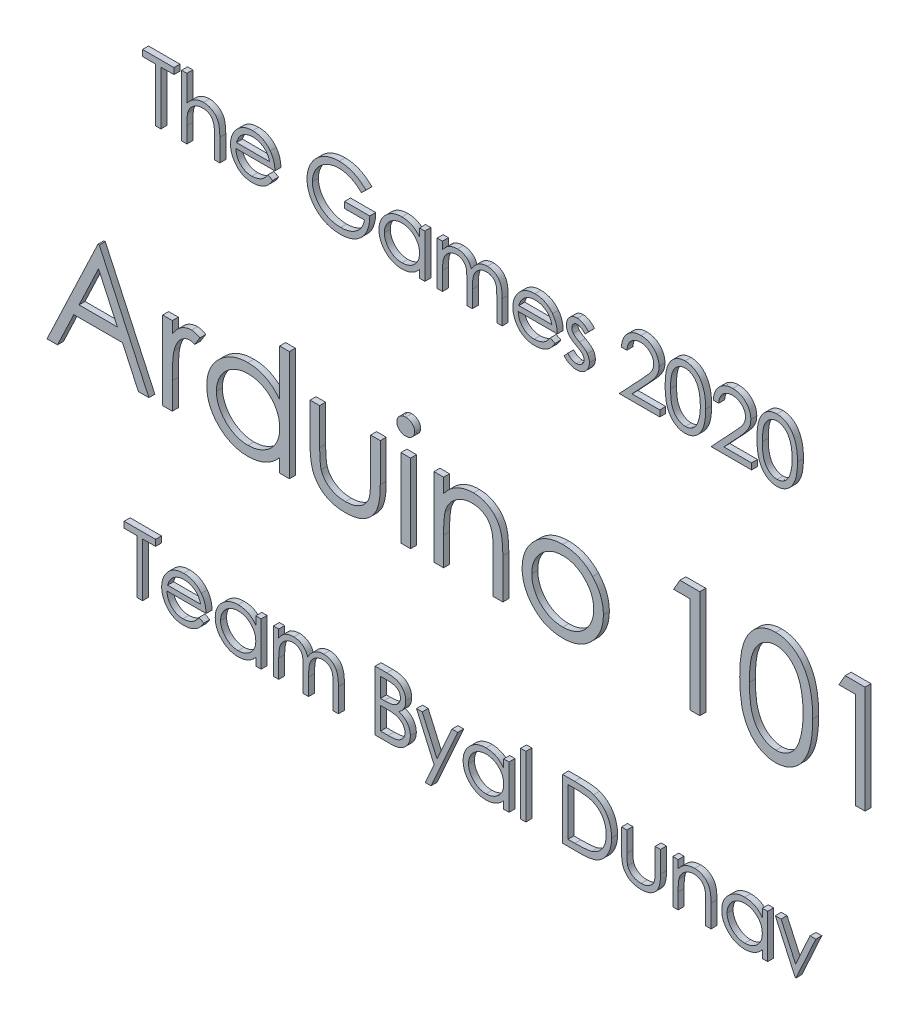
from build123d import *

# Parameters (mm, degrees)
BOSS_EXTRUDE1_DEPTH    = 5
BOSS_EXTRUDE1_2_DEPTH  = 5
BOSS_EXTRUDE1_3_DEPTH  = 5
BOSS_EXTRUDE1_4_DEPTH  = 5
BOSS_EXTRUDE1_5_DEPTH  = 5
BOSS_EXTRUDE1_6_DEPTH  = 5
BOSS_EXTRUDE1_7_DEPTH  = 5
BOSS_EXTRUDE1_8_DEPTH  = 5
BOSS_EXTRUDE1_9_DEPTH  = 5
BOSS_EXTRUDE1_10_DEPTH = 5
BOSS_EXTRUDE1_11_DEPTH = 5
BOSS_EXTRUDE1_12_DEPTH = 5
BOSS_EXTRUDE1_13_DEPTH = 5
BOSS_EXTRUDE1_14_DEPTH = 5
BOSS_EXTRUDE1_15_DEPTH = 5
BOSS_EXTRUDE1_16_DEPTH = 5
BOSS_EXTRUDE1_17_DEPTH = 5
SKETCH1_W              = 8.076923077
SKETCH1_H              = 65.769230769
BOSS_EXTRUDE1_18_DEPTH = 5
BOSS_EXTRUDE1_19_DEPTH = 5
BOSS_EXTRUDE1_20_DEPTH = 5
BOSS_EXTRUDE1_21_DEPTH = 5
BOSS_EXTRUDE1_22_DEPTH = 5
BOSS_EXTRUDE1_23_DEPTH = 5
BOSS_EXTRUDE1_24_DEPTH = 5
BOSS_EXTRUDE1_25_DEPTH = 5
BOSS_EXTRUDE1_26_DEPTH = 5
BOSS_EXTRUDE1_27_DEPTH = 5
BOSS_EXTRUDE1_28_DEPTH = 5
BOSS_EXTRUDE1_29_DEPTH = 5
BOSS_EXTRUDE1_30_DEPTH = 5
SKETCH1_W_2            = 4.487179487
SKETCH1_H_2            = 51.282051282
BOSS_EXTRUDE1_31_DEPTH = 5
BOSS_EXTRUDE1_32_DEPTH = 5
BOSS_EXTRUDE1_33_DEPTH = 5
BOSS_EXTRUDE1_34_DEPTH = 5
BOSS_EXTRUDE1_35_DEPTH = 5
BOSS_EXTRUDE1_36_DEPTH = 5


with BuildPart() as part:
    # Sketch1 → Boss-Extrude1 (new body)
    with BuildSketch(Plane.XY):
        Polygon((-275.320512821, 194.871794872), (-275.320512821, 200), (-249.038461538, 200), (-249.038461538, 194.871794872), (-259.935897436, 194.871794872), (-259.935897436, 150), (-264.423076923, 150), (-264.423076923, 194.871794872), align=None)
    extrude(amount=BOSS_EXTRUDE1_DEPTH)


with BuildPart() as body_2:
    # Sketch1 → Boss-Extrude1 2 (new body)
    with BuildSketch(Plane.XY):
        with BuildLine():
            Line((-242.628205128, 201.282051282), (-238.141025641, 201.282051282))
            Line((-238.141025641, 201.282051282), (-238.141025641, 179.637419872))
            add(Edge.make_bspline(
                [(-238.141025641, 179.637419872), (-237.659349903, 180.239476759), (-236.72150256, 181.411712368), (-235.142986608, 182.941157952), (-233.521974149, 184.266852541), (-231.802476866, 185.322144787), (-230.016040861, 186.155809691), (-228.155131655, 186.747061783), (-226.219403494, 187.110648878), (-224.904758493, 187.156340562), (-224.238782051, 187.179487179)],
                knots=[0, 0, 0, 0, 1.125788106, 2.19196713, 3.20547328, 4.180437432, 5.132270164, 6.079753143, 7.027236121, 8, 8, 8, 8], degree=3))
            add(Edge.make_bspline(
                [(-224.238782051, 187.179487179), (-223.562633582, 187.154552461), (-222.239247933, 187.105749203), (-220.312369894, 186.71984376), (-218.512928824, 186.060451788), (-216.846273927, 185.158065715), (-215.348778254, 184.034168183), (-214.022353051, 182.736575003), (-212.938913068, 181.232661886), (-212.201782826, 179.84328683), (-211.722162714, 178.607018916), (-211.418565194, 177.546497312), (-211.161148075, 176.364755695), (-210.936866135, 175.062402375), (-210.787386398, 173.633185642), (-210.667320427, 172.083553436), (-210.58194251, 170.413594606), (-210.578633874, 169.257591043), (-210.576923077, 168.659855769)],
                knots=[0, 0, 0, 0, 1.235656852, 2.418478516, 3.575258207, 4.727955599, 5.870717718, 6.98870536, 8.107142894, 9.245821548, 9.854588956, 10.528768408, 11.260415777, 12.065282286, 12.943670737, 13.886611085, 14.907229059, 16, 16, 16, 16], degree=3))
            Line((-210.576923077, 168.659855769), (-210.576923077, 150))
            Line((-210.576923077, 150), (-215.064102564, 150))
            Line((-215.064102564, 150), (-215.064102564, 167.1875))
            add(Edge.make_bspline(
                [(-215.064102564, 167.1875), (-215.066821181, 167.684966708), (-215.072021432, 168.636535856), (-215.089212068, 169.998908833), (-215.127586573, 171.234567898), (-215.189598371, 172.339552923), (-215.254817048, 173.315404399), (-215.344578722, 174.160705177), (-215.449010636, 174.876616253), (-215.542850371, 175.307539519), (-215.584935897, 175.500801282)],
                knots=[0, 0, 0, 0, 1.430932559, 2.737130458, 3.918967929, 4.986496826, 5.920444988, 6.731744033, 7.431208747, 8, 8, 8, 8], degree=3))
            add(Edge.make_bspline(
                [(-215.584935897, 175.500801282), (-215.748139399, 176.067862191), (-216.06189718, 177.158033487), (-216.791153997, 178.63892506), (-217.701997012, 179.901564213), (-218.814100749, 180.928911186), (-220.107791664, 181.73479032), (-221.591505437, 182.292901494), (-223.251277844, 182.639297522), (-224.420584583, 182.674144715), (-225.030048077, 182.692307692)],
                knots=[0, 0, 0, 0, 1.090059168, 2.095632401, 3.037101401, 3.955032261, 4.878929692, 5.839099886, 6.873700383, 8, 8, 8, 8], degree=3))
            add(Edge.make_bspline(
                [(-225.030048077, 182.692307692), (-225.391016265, 182.685510173), (-226.105362983, 182.672058059), (-227.164629638, 182.537002366), (-228.192187688, 182.316306386), (-229.197933086, 182.017670119), (-230.160550196, 181.611305312), (-231.108097696, 181.140874036), (-232.013729252, 180.565041822), (-232.893526636, 179.91895943), (-233.712348541, 179.203677148), (-234.474164476, 178.448720648), (-235.153283621, 177.644792587), (-235.768549207, 176.804790929), (-236.299667573, 175.91719388), (-236.763283032, 174.99056076), (-237.156650123, 174.023672965), (-237.352117155, 173.352600655), (-237.449919872, 173.016826923)],
                knots=[0, 0, 0, 0, 1.024319606, 2.027102035, 3.025350316, 4.005802111, 5.00026367, 5.987881639, 7.005602596, 8.042517216, 9.083927026, 10.089214625, 11.084353441, 12.06828073, 13.041928858, 14.016821737, 15.00770877, 16, 16, 16, 16], degree=3))
            add(Edge.make_bspline(
                [(-237.449919872, 173.016826923), (-237.506197404, 172.773670481), (-237.628833073, 172.243802667), (-237.76190212, 171.369883753), (-237.8810135, 170.354364153), (-237.981707068, 169.198784149), (-238.043465445, 167.898909259), (-238.110011742, 166.463609844), (-238.13478337, 164.883895261), (-238.138882697, 163.785388012), (-238.141025641, 163.211137821)],
                knots=[0, 0, 0, 0, 0.607992626, 1.324890765, 2.152360218, 3.099583803, 4.150613268, 5.323148443, 6.60066238, 8, 8, 8, 8], degree=3))
            Line((-238.141025641, 163.211137821), (-238.141025641, 150))
            Line((-238.141025641, 150), (-242.628205128, 150))
            Line((-242.628205128, 150), (-242.628205128, 201.282051282))
        make_face()
    extrude(amount=BOSS_EXTRUDE1_2_DEPTH)


with BuildPart() as body_3:
    # Sketch1 → Boss-Extrude1 3 (new body)
    with BuildSketch(Plane.XY):
        with BuildLine():
            Line((-170.332532051, 161.538461538), (-166.346153846, 159.445112179))
            add(Edge.make_bspline(
                [(-166.346153846, 159.445112179), (-166.663819492, 158.881636018), (-167.281871042, 157.78533455), (-168.344738869, 156.279165114), (-169.458911335, 154.924197745), (-170.674682306, 153.756631255), (-171.95567772, 152.738754327), (-173.30900136, 151.848213974), (-174.741698756, 151.089377969), (-176.253837681, 150.450056142), (-177.858116983, 149.958491941), (-179.55842436, 149.611288785), (-181.358017152, 149.396670661), (-182.591534007, 149.371740079), (-183.223157051, 149.358974359)],
                knots=[0, 0, 0, 0, 1.120438281, 2.179929193, 3.190490725, 4.156257408, 5.095198341, 6.022838206, 6.959905092, 7.901321166, 8.864066838, 9.862729781, 10.905609505, 12, 12, 12, 12], degree=3))
            add(Edge.make_bspline(
                [(-183.223157051, 149.358974359), (-183.925185302, 149.375362578), (-185.29463904, 149.407331246), (-187.288063999, 149.68293788), (-189.164912833, 150.132543005), (-190.925080024, 150.760622169), (-192.56425506, 151.581012513), (-194.085695843, 152.580433681), (-195.497403356, 153.753751606), (-196.754892058, 155.11112937), (-197.886947526, 156.56372876), (-198.885887811, 158.077384252), (-199.720993969, 159.648287459), (-200.400316972, 161.266437802), (-200.9489579, 162.921636282), (-201.331339382, 164.628942961), (-201.551764353, 166.383737022), (-201.585542147, 167.570841818), (-201.602564103, 168.169070513)],
                knots=[0, 0, 0, 0, 1.145258523, 2.234067595, 3.276747158, 4.290159414, 5.277019952, 6.260822364, 7.254936242, 8.264827045, 9.274100331, 10.257902744, 11.220704747, 12.172965371, 13.118907548, 14.062713208, 15.023725156, 16, 16, 16, 16], degree=3))
            add(Edge.make_bspline(
                [(-201.602564103, 168.169070513), (-201.587433512, 168.730425233), (-201.55744668, 169.842956157), (-201.368435432, 171.489606793), (-201.033459816, 173.090013258), (-200.573798046, 174.645505372), (-199.980208814, 176.153478714), (-199.254034254, 177.614851052), (-198.394143143, 179.028067336), (-197.730247803, 179.919540674), (-197.395833333, 180.368589744)],
                knots=[0, 0, 0, 0, 1.024358464, 2.0301432, 3.019427413, 4.004406732, 4.986367066, 5.972626655, 6.978780325, 8, 8, 8, 8], degree=3))
            add(Edge.make_bspline(
                [(-197.395833333, 180.368589744), (-196.942866437, 180.909573602), (-196.051281485, 181.974404323), (-194.543333551, 183.373523262), (-192.910473604, 184.545577194), (-191.173164659, 185.51710771), (-189.31121503, 186.255302667), (-187.349653729, 186.805410984), (-185.266145355, 187.113668285), (-183.841785057, 187.157208765), (-183.112980769, 187.179487179)],
                knots=[0, 0, 0, 0, 1.030682036, 2.02871468, 2.997146059, 3.962720338, 4.930598197, 5.918074684, 6.934738563, 8, 8, 8, 8], degree=3))
            add(Edge.make_bspline(
                [(-183.112980769, 187.179487179), (-182.363729265, 187.160143624), (-180.893868609, 187.122195977), (-178.750552594, 186.770391214), (-176.722542358, 186.212497578), (-174.810649439, 185.424586285), (-173.014679999, 184.408021259), (-171.346307863, 183.148852095), (-169.777000541, 181.685736563), (-168.864020843, 180.560547857), (-168.399439103, 179.987980769)],
                knots=[0, 0, 0, 0, 1.056321875, 2.072262726, 3.055038591, 4.01806755, 4.982017516, 5.957941055, 6.960871419, 8, 8, 8, 8], degree=3))
            add(Edge.make_bspline(
                [(-168.399439103, 179.987980769), (-168.083339984, 179.556501035), (-167.453245797, 178.696413625), (-166.664001511, 177.293968524), (-165.978895868, 175.826674319), (-165.431282139, 174.270812932), (-164.987860693, 172.644818929), (-164.667048997, 170.937068291), (-164.478911589, 169.148069557), (-164.441930198, 167.929118764), (-164.423076923, 167.307692308)],
                knots=[0, 0, 0, 0, 0.94817472, 1.890038105, 2.849395472, 3.817997239, 4.812318967, 5.836947057, 6.897266129, 8, 8, 8, 8], degree=3))
            Line((-164.423076923, 167.307692308), (-197.115384615, 167.307692308))
            add(Edge.make_bspline(
                [(-197.115384615, 167.307692308), (-197.093390238, 166.826257104), (-197.050139181, 165.879534193), (-196.848494279, 164.494237292), (-196.530654654, 163.174618119), (-196.083953759, 161.930574662), (-195.542998827, 160.745858554), (-194.88034573, 159.629258026), (-194.089780673, 158.585859026), (-193.207984968, 157.606328489), (-192.226455034, 156.7340319), (-191.19384436, 155.95329224), (-190.09536486, 155.298926572), (-188.939677953, 154.76778529), (-187.728652451, 154.351980775), (-186.461906806, 154.068154765), (-185.141933716, 153.878053238), (-184.242137515, 153.856915164), (-183.784054487, 153.846153846)],
                knots=[0, 0, 0, 0, 1.094153842, 2.151609401, 3.174256925, 4.172055639, 5.149267565, 6.128595816, 7.11444997, 8.118368179, 9.117203808, 10.09244225, 11.054858984, 12.015122123, 12.976791628, 13.957293641, 14.960065497, 16, 16, 16, 16], degree=3))
            add(Edge.make_bspline(
                [(-183.784054487, 153.846153846), (-183.33618095, 153.85484037), (-182.447513937, 153.872076099), (-181.124073118, 154.039674827), (-179.822079869, 154.310678764), (-178.546922965, 154.680535765), (-177.324482309, 155.131633652), (-176.192403023, 155.67596019), (-175.151257085, 156.278099429), (-174.178157562, 156.966809073), (-173.234286229, 157.809783173), (-172.297964994, 158.861722044), (-171.294012803, 160.105829584), (-170.66559005, 161.042196241), (-170.332532051, 161.538461538)],
                knots=[0, 0, 0, 0, 0.99110716, 1.966546729, 2.947904876, 3.932708344, 4.903319531, 5.828989031, 6.710028674, 7.56322171, 8.463672341, 9.504779593, 10.677557249, 12, 12, 12, 12], degree=3))
        make_face()
        with BuildLine():
            add(Edge.make_bspline(
                [(-168.91025641, 171.794871795), (-169.074493904, 172.390055705), (-169.390598211, 173.535593142), (-170.051117703, 175.121891577), (-170.794996856, 176.531718734), (-171.675307304, 177.754284921), (-172.67271767, 178.840049392), (-173.824791708, 179.788886323), (-175.116733043, 180.637707052), (-176.541863625, 181.354171331), (-178.051031983, 181.964026455), (-179.63112044, 182.37295668), (-181.243374552, 182.653092999), (-182.333864357, 182.679180262), (-182.882612179, 182.692307692)],
                knots=[0, 0, 0, 0, 1.154881502, 2.222775134, 3.210006277, 4.132804581, 5.035138423, 5.962687519, 6.919655026, 7.923214229, 8.944639381, 9.960483929, 10.97369054, 12, 12, 12, 12], degree=3))
            add(Edge.make_bspline(
                [(-182.882612179, 182.692307692), (-183.330461301, 182.683569527), (-184.215764859, 182.666296012), (-185.520065833, 182.502437022), (-186.772632961, 182.231582095), (-187.982708498, 181.860654144), (-189.134435189, 181.366245537), (-190.251503306, 180.786485156), (-191.305508967, 180.078748245), (-191.964670331, 179.539336033), (-192.297676282, 179.266826923)],
                knots=[0, 0, 0, 0, 1.04873581, 2.073130211, 3.073294108, 4.04793562, 5.032784715, 6.005352987, 6.992311501, 8, 8, 8, 8], degree=3))
            add(Edge.make_bspline(
                [(-192.297676282, 179.266826923), (-192.536151739, 179.051193843), (-193.018767942, 178.614805042), (-193.663632535, 177.862959234), (-194.281067859, 177.052222632), (-194.842977184, 176.151577995), (-195.358371276, 175.171281152), (-195.840656664, 174.119600648), (-196.274748266, 172.98855593), (-196.518978409, 172.200378227), (-196.64463141, 171.794871795)],
                knots=[0, 0, 0, 0, 0.879870761, 1.780643979, 2.707998968, 3.669668524, 4.684282772, 5.740141944, 6.837334558, 8, 8, 8, 8], degree=3))
            Line((-196.64463141, 171.794871795), (-168.91025641, 171.794871795))
        make_face(mode=Mode.SUBTRACT)
    extrude(amount=BOSS_EXTRUDE1_3_DEPTH)


with BuildPart() as body_4:
    # Sketch1 → Boss-Extrude1 4 (new body)
    with BuildSketch(Plane.XY):
        with BuildLine():
            Line((-88.141025641, 191.466346154), (-91.987179487, 187.820512821))
            add(Edge.make_bspline(
                [(-91.987179487, 187.820512821), (-92.683163603, 188.475239435), (-94.058535697, 189.769080334), (-96.300824877, 191.447808836), (-98.640305363, 192.885895981), (-101.064769604, 194.055985073), (-103.514177517, 194.989595937), (-105.956017178, 195.654283655), (-108.365241483, 196.078177047), (-109.967630317, 196.128868038), (-110.757211538, 196.153846154)],
                knots=[0, 0, 0, 0, 1.08915593, 2.152340314, 3.188132944, 4.216796309, 5.218260357, 6.173443236, 7.099959455, 8, 8, 8, 8], degree=3))
            add(Edge.make_bspline(
                [(-110.757211538, 196.153846154), (-111.241707252, 196.147937498), (-112.209442118, 196.136135511), (-113.646898461, 195.985503865), (-115.06927899, 195.76886295), (-116.47389863, 195.455407554), (-117.863488435, 195.058135275), (-119.233215466, 194.561200086), (-120.58563482, 193.981839454), (-121.908007406, 193.312375544), (-123.1900146, 192.576949166), (-124.400826537, 191.761970015), (-125.548160807, 190.893558731), (-126.610452597, 189.94997331), (-127.593812407, 188.939760948), (-128.521646292, 187.881713718), (-129.361321948, 186.746924881), (-130.119767161, 185.556273081), (-130.796361709, 184.330670377), (-131.393628189, 183.081913381), (-131.895015162, 181.814144032), (-132.291721666, 180.525771495), (-132.619016722, 179.226763067), (-132.849268253, 177.908124204), (-132.97907857, 176.568442984), (-133.001532569, 175.671339293), (-133.012820513, 175.220352564)],
                knots=[0, 0, 0, 0, 1.02818874, 2.053710826, 3.065248034, 4.081641283, 5.106893873, 6.131558223, 7.173050175, 8.228653731, 9.27666206, 10.308777013, 11.325269123, 12.329503258, 13.32196095, 14.316845687, 15.314881793, 16.315733098, 17.311955233, 18.285320748, 19.252783886, 20.203351036, 21.145449891, 22.095197417, 23.042428769, 24, 24, 24, 24], degree=3))
            add(Edge.make_bspline(
                [(-133.012820513, 175.220352564), (-133.002024538, 174.759340889), (-132.980462067, 173.83857641), (-132.842457502, 172.464375373), (-132.586339782, 171.11058391), (-132.243943941, 169.772753437), (-131.815646574, 168.448592753), (-131.281751344, 167.143842612), (-130.649385623, 165.858551309), (-129.917434879, 164.604299638), (-129.114774829, 163.382542163), (-128.215587958, 162.231691851), (-127.260436766, 161.136423605), (-126.214523911, 160.121055551), (-125.111387594, 159.158428461), (-123.918069365, 158.275063862), (-122.658034215, 157.453946386), (-121.32935976, 156.705424681), (-119.946462868, 156.036731314), (-118.528509252, 155.442104227), (-117.070969029, 154.952399408), (-115.581502034, 154.553283637), (-114.061883868, 154.226136533), (-112.504400972, 154.015672529), (-110.920505138, 153.862946373), (-109.852810394, 153.851779658), (-109.314903846, 153.846153846)],
                knots=[0, 0, 0, 0, 0.93586088, 1.869166235, 2.799637598, 3.729985548, 4.670839027, 5.622275134, 6.589130586, 7.576015415, 8.568469353, 9.55398029, 10.53834874, 11.515998671, 12.510579167, 13.508179873, 14.527009472, 15.561807829, 16.601455013, 17.643573243, 18.680854198, 19.719860599, 20.772568776, 21.833555941, 22.908541556, 24, 24, 24, 24], degree=3))
            add(Edge.make_bspline(
                [(-109.314903846, 153.846153846), (-108.666641743, 153.859704936), (-107.393673782, 153.886314704), (-105.522438886, 154.093461695), (-103.725252161, 154.416987319), (-102.007163544, 154.890785843), (-100.366177533, 155.495124057), (-98.796278372, 156.223629578), (-97.309826105, 157.104244707), (-95.902352197, 158.098157094), (-94.605820976, 159.205511844), (-93.436476346, 160.400432632), (-92.412969357, 161.677119299), (-91.520045082, 163.028052374), (-90.78135002, 164.464413875), (-90.175024376, 165.979164767), (-89.710263067, 167.572986366), (-89.519477712, 168.67429539), (-89.423076923, 169.230769231)],
                knots=[0, 0, 0, 0, 1.13008108, 2.219097802, 3.278683437, 4.311054135, 5.322181354, 6.324827112, 7.324222904, 8.330512327, 9.32562643, 10.293043162, 11.24128371, 12.174520618, 13.111833804, 14.052305215, 15.015860969, 16, 16, 16, 16], degree=3))
            Line((-89.423076923, 169.230769231), (-106.08974359, 169.230769231))
            Line((-106.08974359, 169.230769231), (-106.08974359, 174.358974359))
            Line((-106.08974359, 174.358974359), (-84.935897436, 174.358974359))
            add(Edge.make_bspline(
                [(-84.935897436, 174.358974359), (-84.960266698, 173.40315309), (-85.007961747, 171.532438208), (-85.342517685, 168.804291482), (-85.882753575, 166.227553006), (-86.62075803, 163.799509125), (-87.576119177, 161.523600657), (-88.738583869, 159.397516855), (-90.126757027, 157.434992842), (-91.691191906, 155.620007077), (-93.446905589, 154.001018331), (-95.346457303, 152.578076361), (-97.392985422, 151.37946757), (-99.5845541, 150.40431525), (-101.913988864, 149.64325818), (-104.386680004, 149.103664227), (-106.999274299, 148.780379036), (-108.789798255, 148.739073616), (-109.705528846, 148.717948718)],
                knots=[0, 0, 0, 0, 1.140356446, 2.231883559, 3.274166699, 4.278491846, 5.25512956, 6.21435461, 7.1637429, 8.11826594, 9.068280886, 10.0076534, 10.945064095, 11.891975133, 12.864533718, 13.863980011, 14.907571808, 16, 16, 16, 16], degree=3))
            add(Edge.make_bspline(
                [(-109.705528846, 148.717948718), (-110.269959351, 148.726079021), (-111.383198221, 148.7421146), (-113.027354336, 148.856076706), (-114.626177487, 149.03151351), (-116.179434757, 149.296443846), (-117.692839645, 149.620938905), (-119.158833716, 150.036463459), (-120.583001459, 150.517444878), (-121.967544111, 151.064525928), (-123.299894779, 151.698406737), (-124.585987879, 152.402830159), (-125.832932532, 153.174163884), (-127.032234889, 154.025747394), (-128.190143767, 154.951211111), (-129.299192962, 155.952409953), (-130.36559122, 157.026283092), (-131.033597842, 157.788840372), (-131.370192308, 158.173076923)],
                knots=[0, 0, 0, 0, 1.107784379, 2.184907829, 3.233506516, 4.263428166, 5.276301166, 6.270063455, 7.25232949, 8.225834625, 9.190232166, 10.146266622, 11.1027726, 12.066435141, 13.031522626, 14.010570082, 14.99756817, 16, 16, 16, 16], degree=3))
            add(Edge.make_bspline(
                [(-131.370192308, 158.173076923), (-131.858562764, 158.78265768), (-132.82719723, 159.991700783), (-134.074028039, 161.928842846), (-135.136905222, 163.934583705), (-135.999302681, 166.014506968), (-136.672703915, 168.166667151), (-137.155650383, 170.388314169), (-137.438611657, 172.682308891), (-137.479376477, 174.234669815), (-137.5, 175.020032051)],
                knots=[0, 0, 0, 0, 1.023165419, 2.029347347, 3.013907458, 3.994755782, 4.975994455, 5.96558838, 6.970761222, 8, 8, 8, 8], degree=3))
            add(Edge.make_bspline(
                [(-137.5, 175.020032051), (-137.492396598, 175.608121375), (-137.477286429, 176.776825768), (-137.294064769, 178.51193016), (-137.031187369, 180.216225762), (-136.644800875, 181.888319423), (-136.157711379, 183.529327877), (-135.549804436, 185.140013075), (-134.842020208, 186.721325527), (-134.019370263, 188.262380784), (-133.103877985, 189.742729538), (-132.110303409, 191.156412443), (-131.024537691, 192.4776848), (-129.864311983, 193.723279775), (-128.615783552, 194.877549018), (-127.290648928, 195.95117917), (-125.887886887, 196.945610396), (-124.403084316, 197.845179464), (-122.858403109, 198.653231185), (-121.257545946, 199.361648495), (-119.601001504, 199.94712443), (-117.901180395, 200.443892711), (-116.1452161, 200.811251862), (-114.345851288, 201.07766251), (-112.49370683, 201.259956791), (-111.241763554, 201.274617588), (-110.606971154, 201.282051282)],
                knots=[0, 0, 0, 0, 1.008945113, 2.00506715, 2.99143336, 3.967273523, 4.948097931, 5.927297278, 6.919902385, 7.919676788, 8.923139349, 9.905703106, 10.883022732, 11.856032218, 12.825136022, 13.798837087, 14.781400844, 15.773989409, 16.776158564, 17.77167057, 18.775803737, 19.789618931, 20.80898985, 21.851988756, 22.910860228, 24, 24, 24, 24], degree=3))
            add(Edge.make_bspline(
                [(-110.606971154, 201.282051282), (-110.089281959, 201.273772829), (-109.06276512, 201.257357628), (-107.535254658, 201.143576941), (-106.031354449, 200.963235783), (-104.548834593, 200.717138831), (-103.092743647, 200.381943253), (-101.65893357, 199.980824901), (-100.245325909, 199.513798864), (-98.856350921, 198.956815345), (-97.482669263, 198.324620703), (-96.116642971, 197.613000383), (-94.762939457, 196.809786031), (-93.419211151, 195.912592666), (-92.076984609, 194.936829554), (-90.757489719, 193.854589216), (-89.428876229, 192.708549847), (-88.574564598, 191.884518648), (-88.141025641, 191.466346154)],
                knots=[0, 0, 0, 0, 0.985871117, 1.954866573, 2.915460327, 3.869826059, 4.81536089, 5.759505086, 6.70452669, 7.649098992, 8.607881297, 9.583363685, 10.581137262, 11.603961102, 12.659522466, 13.73993555, 14.853081303, 16, 16, 16, 16], degree=3))
        make_face()
    extrude(amount=BOSS_EXTRUDE1_4_DEPTH)


with BuildPart() as body_5:
    # Sketch1 → Boss-Extrude1 5 (new body)
    with BuildSketch(Plane.XY):
        with BuildLine():
            Line((-38.782051282, 186.538461538), (-38.782051282, 150))
            Line((-38.782051282, 150), (-43.269230769, 150))
            Line((-43.269230769, 150), (-43.269230769, 156.320112179))
            add(Edge.make_bspline(
                [(-43.269230769, 156.320112179), (-43.775213492, 155.74811798), (-44.762645139, 154.631864107), (-46.411803967, 153.173547358), (-48.159920795, 151.968142764), (-49.998511097, 150.99457254), (-51.925914573, 150.263257449), (-53.937858677, 149.743455176), (-56.035164118, 149.409257531), (-57.467340615, 149.37588579), (-58.193108974, 149.358974359)],
                knots=[0, 0, 0, 0, 1.074387032, 2.096679803, 3.090159297, 4.057316773, 5.018401886, 5.985159533, 6.978961417, 8, 8, 8, 8], degree=3))
            add(Edge.make_bspline(
                [(-58.193108974, 149.358974359), (-58.838365458, 149.376493963), (-60.110839813, 149.411043397), (-61.982683772, 149.679076306), (-63.784001622, 150.109513758), (-65.516495517, 150.708097894), (-67.168954737, 151.502109631), (-68.755527547, 152.452698889), (-70.267994576, 153.584710748), (-71.683302275, 154.878825438), (-72.986616566, 156.284468112), (-74.130349032, 157.783690211), (-75.083964459, 159.370008838), (-75.881394183, 161.023339607), (-76.495627675, 162.756409886), (-76.92382245, 164.563226571), (-77.191543118, 166.441653336), (-77.22607827, 167.72078938), (-77.243589744, 168.369391026)],
                knots=[0, 0, 0, 0, 1.033919861, 2.038935746, 3.024066025, 3.998881131, 4.97069526, 5.957263378, 6.95902576, 7.993208707, 9.027059324, 10.027763471, 11.009749337, 11.988697705, 12.965288445, 13.950418724, 14.960734635, 16, 16, 16, 16], degree=3))
            add(Edge.make_bspline(
                [(-77.243589744, 168.369391026), (-77.225690152, 169.004586791), (-77.190303626, 170.260334553), (-76.9266862, 172.107173095), (-76.483386076, 173.886005391), (-75.861273967, 175.59110458), (-75.063531753, 177.224533868), (-74.09313051, 178.787448511), (-72.950000157, 180.284154189), (-71.632108628, 181.67945743), (-70.204469054, 182.968323348), (-68.67720147, 184.088452568), (-67.088297451, 185.055836123), (-65.413111586, 185.822314356), (-63.67643866, 186.442444421), (-61.862818007, 186.871486822), (-59.979795454, 187.124305697), (-58.701359853, 187.160916613), (-58.052884615, 187.179487179)],
                knots=[0, 0, 0, 0, 1.020392517, 2.01726096, 2.990465484, 3.961182959, 4.928053699, 5.906110375, 6.912531644, 7.948652711, 8.985773172, 9.998621852, 10.987621588, 11.969261332, 12.953316658, 13.946091881, 14.958173133, 16, 16, 16, 16], degree=3))
            add(Edge.make_bspline(
                [(-58.052884615, 187.179487179), (-57.307172343, 187.158947872), (-55.844865772, 187.118671259), (-53.705894211, 186.78348944), (-51.682401669, 186.217225623), (-49.758768069, 185.446975652), (-47.941901125, 184.423422379), (-46.249001349, 183.132280079), (-44.662351587, 181.581691693), (-43.742633135, 180.390685344), (-43.269230769, 179.777644231)],
                knots=[0, 0, 0, 0, 1.038897134, 2.037228247, 3.008116434, 3.962042015, 4.918381754, 5.904844433, 6.921570401, 8, 8, 8, 8], degree=3))
            Line((-43.269230769, 179.777644231), (-43.269230769, 186.538461538))
            Line((-43.269230769, 186.538461538), (-38.782051282, 186.538461538))
        make_face()
        with BuildLine():
            add(Edge.make_bspline(
                [(-57.992788462, 182.692307692), (-58.648707574, 182.66897001), (-59.943387574, 182.622905138), (-61.844016174, 182.263283779), (-63.662779233, 181.664932431), (-65.390580294, 180.846619557), (-67.000126246, 179.817637605), (-68.438607257, 178.573046415), (-69.717788705, 177.146803356), (-70.793621052, 175.545344636), (-71.67062815, 173.828514764), (-72.287300035, 172.033879934), (-72.69400357, 170.193808826), (-72.735553863, 168.945770457), (-72.756410256, 168.319310897)],
                knots=[0, 0, 0, 0, 1.031046209, 2.035121221, 3.029706178, 4.034933723, 5.034054252, 6.02443088, 7.017295772, 8.038157696, 9.050218397, 10.03989886, 11.016116709, 12, 12, 12, 12], degree=3))
            add(Edge.make_bspline(
                [(-72.756410256, 168.319310897), (-72.729768923, 167.696595081), (-72.676590682, 166.453604282), (-72.294437905, 164.611024614), (-71.653296856, 162.815966871), (-70.778410246, 161.083666963), (-69.682887035, 159.475322672), (-68.413049142, 158.02189235), (-66.956616552, 156.772041089), (-65.343366451, 155.725790037), (-63.620395445, 154.880611167), (-61.808482138, 154.292530603), (-59.941687307, 153.912848023), (-58.672368252, 153.868498354), (-58.032852564, 153.846153846)],
                knots=[0, 0, 0, 0, 0.979072187, 1.954306742, 2.945804271, 3.96968567, 4.997920485, 5.998718438, 6.996577872, 8.005894225, 9.015743152, 10.005417472, 10.995077863, 12, 12, 12, 12], degree=3))
            add(Edge.make_bspline(
                [(-58.032852564, 153.846153846), (-57.38361681, 153.869867617), (-56.092351289, 153.917031954), (-54.186084033, 154.278192887), (-52.336155993, 154.874890006), (-50.567767016, 155.702020388), (-48.920393714, 156.727125472), (-47.441852605, 157.927226772), (-46.191624486, 159.322986546), (-45.131730063, 160.856935875), (-44.300652682, 162.538535824), (-43.695280408, 164.329024264), (-43.337367468, 166.228463523), (-43.292257045, 167.526519622), (-43.269230769, 168.189102564)],
                knots=[0, 0, 0, 0, 1.01762866, 2.023962475, 3.030623092, 4.058876274, 5.077231937, 6.066672613, 7.034107872, 8.005628644, 8.981990164, 9.965428785, 10.961468474, 12, 12, 12, 12], degree=3))
            add(Edge.make_bspline(
                [(-43.269230769, 168.189102564), (-43.282940146, 168.693928714), (-43.309924538, 169.687586334), (-43.516075531, 171.14655087), (-43.844003051, 172.542746956), (-44.306091194, 173.877642514), (-44.913109543, 175.14385702), (-45.645220484, 176.350482166), (-46.515298338, 177.491242329), (-47.509336853, 178.550429057), (-48.597411176, 179.516521375), (-49.748761756, 180.378867671), (-50.97702957, 181.08727871), (-52.261558668, 181.673582588), (-53.604577732, 182.140141873), (-55.017015158, 182.451394641), (-56.483857829, 182.665113513), (-57.484515763, 182.683147524), (-57.992788462, 182.692307692)],
                knots=[0, 0, 0, 0, 1.050140795, 2.067009409, 3.05949893, 4.030605086, 5.00011959, 5.97591094, 6.962425594, 7.979863591, 8.993523472, 9.986985069, 10.967611495, 11.937549037, 12.921786183, 13.919465291, 14.943216303, 16, 16, 16, 16], degree=3))
        make_face(mode=Mode.SUBTRACT)
    extrude(amount=BOSS_EXTRUDE1_5_DEPTH)


with BuildPart() as body_6:
    # Sketch1 → Boss-Extrude1 6 (new body)
    with BuildSketch(Plane.XY):
        with BuildLine():
            Line((-28.525641026, 186.538461538), (-24.038461538, 186.538461538))
            Line((-24.038461538, 186.538461538), (-24.038461538, 180.188301282))
            add(Edge.make_bspline(
                [(-24.038461538, 180.188301282), (-23.634405111, 180.74383845), (-22.86019426, 181.808300922), (-21.590684938, 183.211019268), (-20.32245476, 184.401421478), (-19.409120735, 185.026319643), (-18.970352564, 185.326522436)],
                knots=[0, 0, 0, 0, 1.134379233, 2.173579362, 3.122582517, 4, 4, 4, 4], degree=3))
            add(Edge.make_bspline(
                [(-18.970352564, 185.326522436), (-18.372285961, 185.612313368), (-17.18660168, 186.17890213), (-15.309184181, 186.753667258), (-13.388117473, 187.106882991), (-12.090857274, 187.155188326), (-11.438301282, 187.179487179)],
                knots=[0, 0, 0, 0, 1.014936303, 2.012140481, 3.000054389, 4, 4, 4, 4], degree=3))
            add(Edge.make_bspline(
                [(-11.438301282, 187.179487179), (-10.99697276, 187.164554454), (-10.123607345, 187.135003393), (-8.829548915, 186.942717177), (-7.574425889, 186.610343276), (-6.365654041, 186.147381505), (-5.226787194, 185.586714549), (-4.182655798, 184.928861579), (-3.245167109, 184.190331931), (-2.414794948, 183.337775745), (-1.668094585, 182.347252909), (-0.981253919, 181.192049353), (-0.346608028, 179.846225624), (0.005124955, 178.869560753), (0.190304487, 178.35536859)],
                knots=[0, 0, 0, 0, 1.009824226, 1.998387844, 2.986035974, 3.974953746, 4.955485308, 5.885931332, 6.793869504, 7.679848016, 8.601185859, 9.625726857, 10.749998409, 12, 12, 12, 12], degree=3))
            add(Edge.make_bspline(
                [(0.190304487, 178.35536859), (0.386179507, 178.708574579), (0.771634037, 179.403634364), (1.418857424, 180.387323825), (2.096968802, 181.307420851), (2.811747274, 182.164655485), (3.560669943, 182.954794491), (4.347261376, 183.680450229), (5.167043968, 184.344738996), (6.30693311, 185.120784132), (7.789970358, 185.945086723), (9.659800568, 186.65977878), (11.604803019, 187.101437757), (12.925055852, 187.153298797), (13.591746795, 187.179487179)],
                knots=[0, 0, 0, 0, 0.86119277, 1.694706429, 2.50939023, 3.298075842, 4.073795165, 4.829715201, 5.57930267, 6.321991688, 7.768977793, 9.186738141, 10.579381044, 12, 12, 12, 12], degree=3))
            add(Edge.make_bspline(
                [(13.591746795, 187.179487179), (14.204339121, 187.156384024), (15.403241782, 187.111168907), (17.148631292, 186.756119288), (18.776371368, 186.146438614), (20.283186741, 185.314529521), (21.642612647, 184.269112616), (22.824274207, 183.025272079), (23.820993683, 181.591806036), (24.472117107, 180.243349054), (24.913763739, 179.0528443), (25.186067087, 178.038468709), (25.426634159, 176.922017953), (25.626366234, 175.702157075), (25.77234555, 174.374576956), (25.880498629, 172.941450158), (25.953699679, 171.401662849), (25.95887214, 170.33929856), (25.961538462, 169.791666667)],
                knots=[0, 0, 0, 0, 1.209669288, 2.367440248, 3.500751976, 4.631527125, 5.755587489, 6.87532382, 8.007944318, 9.190864318, 9.82315674, 10.514484317, 11.263564316, 12.079023757, 12.955305781, 13.901327259, 14.918167583, 16, 16, 16, 16], degree=3))
            Line((25.961538462, 169.791666667), (25.961538462, 150))
            Line((25.961538462, 150), (21.474358974, 150))
            Line((21.474358974, 150), (21.474358974, 169.811698718))
            add(Edge.make_bspline(
                [(21.474358974, 169.811698718), (21.47324636, 170.279135488), (21.471108086, 171.177477872), (21.432627635, 172.466798604), (21.360123148, 173.64206085), (21.275342594, 174.701662109), (21.157573889, 175.648073373), (21.00548915, 176.479393639), (20.844379437, 177.202162372), (20.576722421, 178.003391624), (20.148895398, 178.887251774), (19.497217112, 179.840445713), (18.676215594, 180.67017143), (17.728213357, 181.390433099), (16.648949862, 181.976056543), (15.459453816, 182.394285254), (14.167110222, 182.653183517), (13.272498959, 182.678983739), (12.810496795, 182.692307692)],
                knots=[0, 0, 0, 0, 1.253487763, 2.409012846, 3.458416907, 4.410876679, 5.259312806, 6.014470957, 6.676830364, 7.243083969, 8.276244668, 9.299465089, 10.325150304, 11.392391894, 12.482080715, 13.603491619, 14.762376348, 16, 16, 16, 16], degree=3))
            add(Edge.make_bspline(
                [(12.810496795, 182.692307692), (12.243783161, 182.672076872), (11.123741573, 182.632093081), (9.488806055, 182.223894896), (7.917791532, 181.608462744), (6.457575348, 180.716570499), (5.114321196, 179.647879587), (3.958612942, 178.377171076), (3.003867433, 176.939600692), (2.357382062, 175.608933516), (1.948963473, 174.413655746), (1.679293248, 173.369407574), (1.469530513, 172.182528034), (1.272808667, 170.86099245), (1.144412553, 169.395704159), (1.02772152, 167.793441288), (0.973137765, 166.049384725), (0.96550264, 164.84043203), (0.961538462, 164.212740385)],
                knots=[0, 0, 0, 0, 1.090531906, 2.155305635, 3.229839962, 4.33261226, 5.44038871, 6.529323825, 7.629011124, 8.757537029, 9.370236727, 10.061839251, 10.834451254, 11.692844982, 12.636905849, 13.66920014, 14.789842145, 16, 16, 16, 16], degree=3))
            Line((0.961538462, 164.212740385), (0.961538462, 150))
            Line((0.961538462, 150), (-3.525641026, 150))
            Line((-3.525641026, 150), (-3.525641026, 168.579727564))
            add(Edge.make_bspline(
                [(-3.525641026, 168.579727564), (-3.526775754, 169.103917832), (-3.528958857, 170.11240722), (-3.567191961, 171.558602582), (-3.639857986, 172.874046583), (-3.723865819, 174.057210352), (-3.844725513, 175.10594362), (-3.982007828, 176.025868735), (-4.144130836, 176.814679465), (-4.412557759, 177.679870677), (-4.822764449, 178.633026719), (-5.482596763, 179.649327022), (-6.305562197, 180.538871272), (-7.270860424, 181.298281964), (-8.356655884, 181.926017411), (-9.556418752, 182.37829958), (-10.859346079, 182.641503717), (-11.75759902, 182.67505367), (-12.219551282, 182.692307692)],
                knots=[0, 0, 0, 0, 1.320475261, 2.540461679, 3.643808994, 4.639130445, 5.527981419, 6.302341397, 6.981980563, 7.553956391, 8.582137848, 9.585246428, 10.591171744, 11.620968678, 12.668337649, 13.738356861, 14.836885341, 16, 16, 16, 16], degree=3))
            add(Edge.make_bspline(
                [(-12.219551282, 182.692307692), (-12.762640017, 182.670443978), (-13.84499658, 182.626870371), (-15.435024718, 182.234666459), (-16.970534484, 181.620322534), (-18.427030181, 180.768039404), (-19.7652323, 179.712338281), (-20.936778975, 178.470696913), (-21.921672197, 177.058567863), (-22.574983839, 175.741931913), (-22.996390612, 174.576599414), (-23.276323964, 173.58587159), (-23.516890047, 172.485868043), (-23.695661786, 171.273195028), (-23.868239152, 169.955750826), (-23.951529281, 168.526972402), (-24.032551598, 166.988085434), (-24.036443236, 165.925620502), (-24.038461538, 165.374599359)],
                knots=[0, 0, 0, 0, 1.098833095, 2.189935336, 3.297829714, 4.440610912, 5.596351641, 6.740013378, 7.886572111, 9.072425424, 9.705826452, 10.395263256, 11.156850408, 11.985370555, 12.878090359, 13.847760091, 14.883794034, 16, 16, 16, 16], degree=3))
            Line((-24.038461538, 165.374599359), (-24.038461538, 150))
            Line((-24.038461538, 150), (-28.525641026, 150))
            Line((-28.525641026, 150), (-28.525641026, 186.538461538))
        make_face()
    extrude(amount=BOSS_EXTRUDE1_6_DEPTH)


with BuildPart() as body_7:
    # Sketch1 → Boss-Extrude1 7 (new body)
    with BuildSketch(Plane.XY):
        with BuildLine():
            Line((66.205929487, 161.538461538), (70.192307692, 159.445112179))
            add(Edge.make_bspline(
                [(70.192307692, 159.445112179), (69.874642046, 158.881636018), (69.256590496, 157.78533455), (68.193722669, 156.279165114), (67.079550204, 154.924197745), (65.863779232, 153.756631255), (64.582783819, 152.738754327), (63.229460179, 151.848213974), (61.796762783, 151.089377969), (60.284623857, 150.450056142), (58.680344555, 149.958491941), (56.980037178, 149.611288785), (55.180444387, 149.396670661), (53.946927532, 149.371740079), (53.315304487, 149.358974359)],
                knots=[0, 0, 0, 0, 1.120438281, 2.179929193, 3.190490725, 4.156257408, 5.095198341, 6.022838206, 6.959905092, 7.901321166, 8.864066838, 9.862729781, 10.905609505, 12, 12, 12, 12], degree=3))
            add(Edge.make_bspline(
                [(53.315304487, 149.358974359), (52.613276237, 149.375362578), (51.243822499, 149.407331246), (49.25039754, 149.68293788), (47.373548706, 150.132543005), (45.613381515, 150.760622169), (43.974206478, 151.581012513), (42.452765695, 152.580433681), (41.041058183, 153.753751606), (39.78356948, 155.11112937), (38.651514013, 156.56372876), (37.652573727, 158.077384252), (36.81746757, 159.648287459), (36.138144567, 161.266437802), (35.589503639, 162.921636282), (35.207122156, 164.628942961), (34.986697185, 166.383737022), (34.952919392, 167.570841818), (34.935897436, 168.169070513)],
                knots=[0, 0, 0, 0, 1.145258523, 2.234067595, 3.276747158, 4.290159414, 5.277019952, 6.260822364, 7.254936242, 8.264827045, 9.274100331, 10.257902744, 11.220704747, 12.172965371, 13.118907548, 14.062713208, 15.023725156, 16, 16, 16, 16], degree=3))
            add(Edge.make_bspline(
                [(34.935897436, 168.169070513), (34.951028026, 168.730425233), (34.981014858, 169.842956157), (35.170026107, 171.489606793), (35.505001722, 173.090013258), (35.964663493, 174.645505372), (36.558252724, 176.153478714), (37.284427284, 177.614851052), (38.144318396, 179.028067336), (38.808213735, 179.919540674), (39.142628205, 180.368589744)],
                knots=[0, 0, 0, 0, 1.024358464, 2.0301432, 3.019427413, 4.004406732, 4.986367066, 5.972626655, 6.978780325, 8, 8, 8, 8], degree=3))
            add(Edge.make_bspline(
                [(39.142628205, 180.368589744), (39.595595102, 180.909573602), (40.487180053, 181.974404323), (41.995127987, 183.373523262), (43.627987935, 184.545577194), (45.365296879, 185.51710771), (47.227246509, 186.255302667), (49.188807809, 186.805410984), (51.272316184, 187.113668285), (52.696676481, 187.157208765), (53.425480769, 187.179487179)],
                knots=[0, 0, 0, 0, 1.030682036, 2.02871468, 2.997146059, 3.962720338, 4.930598197, 5.918074684, 6.934738563, 8, 8, 8, 8], degree=3))
            add(Edge.make_bspline(
                [(53.425480769, 187.179487179), (54.174732274, 187.160143624), (55.64459293, 187.122195977), (57.787908945, 186.770391214), (59.815919181, 186.212497578), (61.7278121, 185.424586285), (63.523781539, 184.408021259), (65.192153676, 183.148852095), (66.761460998, 181.685736563), (67.674440696, 180.560547857), (68.139022436, 179.987980769)],
                knots=[0, 0, 0, 0, 1.056321875, 2.072262726, 3.055038591, 4.01806755, 4.982017516, 5.957941055, 6.960871419, 8, 8, 8, 8], degree=3))
            add(Edge.make_bspline(
                [(68.139022436, 179.987980769), (68.455121555, 179.556501035), (69.085215742, 178.696413625), (69.874460028, 177.293968524), (70.559565671, 175.826674319), (71.107179399, 174.270812932), (71.550600845, 172.644818929), (71.871412541, 170.937068291), (72.05954995, 169.148069557), (72.09653134, 167.929118764), (72.115384615, 167.307692308)],
                knots=[0, 0, 0, 0, 0.94817472, 1.890038105, 2.849395472, 3.817997239, 4.812318967, 5.836947057, 6.897266129, 8, 8, 8, 8], degree=3))
            Line((72.115384615, 167.307692308), (39.423076923, 167.307692308))
            add(Edge.make_bspline(
                [(39.423076923, 167.307692308), (39.445071301, 166.826257104), (39.488322357, 165.879534193), (39.689967259, 164.494237292), (40.007806885, 163.174618119), (40.45450778, 161.930574662), (40.995462712, 160.745858554), (41.658115809, 159.629258026), (42.448680865, 158.585859026), (43.330476571, 157.606328489), (44.312006504, 156.7340319), (45.344617179, 155.95329224), (46.443096679, 155.298926572), (47.598783586, 154.76778529), (48.809809088, 154.351980775), (50.076554732, 154.068154765), (51.396527823, 153.878053238), (52.296324023, 153.856915164), (52.754407051, 153.846153846)],
                knots=[0, 0, 0, 0, 1.094153842, 2.151609401, 3.174256925, 4.172055639, 5.149267565, 6.128595816, 7.11444997, 8.118368179, 9.117203808, 10.09244225, 11.054858984, 12.015122123, 12.976791628, 13.957293641, 14.960065497, 16, 16, 16, 16], degree=3))
            add(Edge.make_bspline(
                [(52.754407051, 153.846153846), (53.202280588, 153.85484037), (54.090947602, 153.872076099), (55.414388421, 154.039674827), (56.716381669, 154.310678764), (57.991538573, 154.680535765), (59.213979229, 155.131633652), (60.346058516, 155.67596019), (61.387204453, 156.278099429), (62.360303976, 156.966809073), (63.30417531, 157.809783173), (64.240496544, 158.861722044), (65.244448735, 160.105829584), (65.872871489, 161.042196241), (66.205929487, 161.538461538)],
                knots=[0, 0, 0, 0, 0.99110716, 1.966546729, 2.947904876, 3.932708344, 4.903319531, 5.828989031, 6.710028674, 7.56322171, 8.463672341, 9.504779593, 10.677557249, 12, 12, 12, 12], degree=3))
        make_face()
        with BuildLine():
            add(Edge.make_bspline(
                [(67.628205128, 171.794871795), (67.463967635, 172.390055705), (67.147863328, 173.535593142), (66.487343836, 175.121891577), (65.743464683, 176.531718734), (64.863154235, 177.754284921), (63.865743868, 178.840049392), (62.713669831, 179.788886323), (61.421728495, 180.637707052), (59.996597914, 181.354171331), (58.487429556, 181.964026455), (56.907341099, 182.37295668), (55.295086987, 182.653092999), (54.204597182, 182.679180262), (53.655849359, 182.692307692)],
                knots=[0, 0, 0, 0, 1.154881502, 2.222775134, 3.210006277, 4.132804581, 5.035138423, 5.962687519, 6.919655026, 7.923214229, 8.944639381, 9.960483929, 10.97369054, 12, 12, 12, 12], degree=3))
            add(Edge.make_bspline(
                [(53.655849359, 182.692307692), (53.208000237, 182.683569527), (52.322696679, 182.666296012), (51.018395705, 182.502437022), (49.765828578, 182.231582095), (48.555753041, 181.860654144), (47.404026349, 181.366245537), (46.286958232, 180.786485156), (45.232952571, 180.078748245), (44.573791207, 179.539336033), (44.240785256, 179.266826923)],
                knots=[0, 0, 0, 0, 1.04873581, 2.073130211, 3.073294108, 4.04793562, 5.032784715, 6.005352987, 6.992311501, 8, 8, 8, 8], degree=3))
            add(Edge.make_bspline(
                [(44.240785256, 179.266826923), (44.0023098, 179.051193843), (43.519693597, 178.614805042), (42.874829004, 177.862959234), (42.25739368, 177.052222632), (41.695484355, 176.151577995), (41.180090262, 175.171281152), (40.697804874, 174.119600648), (40.263713273, 172.98855593), (40.01948313, 172.200378227), (39.893830128, 171.794871795)],
                knots=[0, 0, 0, 0, 0.879870761, 1.780643979, 2.707998968, 3.669668524, 4.684282772, 5.740141944, 6.837334558, 8, 8, 8, 8], degree=3))
            Line((39.893830128, 171.794871795), (67.628205128, 171.794871795))
        make_face(mode=Mode.SUBTRACT)
    extrude(amount=BOSS_EXTRUDE1_7_DEPTH)


with BuildPart() as body_8:
    # Sketch1 → Boss-Extrude1 8 (new body)
    with BuildSketch(Plane.XY):
        with BuildLine():
            Line((98.397435897, 181.981169872), (95.352564103, 178.846153846))
            add(Edge.make_bspline(
                [(95.352564103, 178.846153846), (95.089842624, 179.150627365), (94.583346541, 179.737616466), (93.780039669, 180.522431702), (92.979702476, 181.18153083), (92.193290853, 181.737991671), (91.401029866, 182.158693765), (90.61221675, 182.465763222), (89.826034771, 182.655789017), (89.300519983, 182.680280998), (89.042467949, 182.692307692)],
                knots=[0, 0, 0, 0, 1.26578478, 2.440284043, 3.530471711, 4.527705817, 5.468200915, 6.346673037, 7.188140097, 8, 8, 8, 8], degree=3))
            add(Edge.make_bspline(
                [(89.042467949, 182.692307692), (88.726190951, 182.676952364), (88.10380258, 182.646735251), (87.212005176, 182.345114818), (86.384139104, 181.88213284), (85.667610818, 181.225438789), (85.060643961, 180.47166352), (84.617591375, 179.628858879), (84.346648752, 178.722458254), (84.312295437, 178.093460288), (84.294871795, 177.774439103)],
                knots=[0, 0, 0, 0, 0.99966794, 1.967205029, 2.953328237, 3.988086729, 5.028030931, 6.008226631, 6.989793394, 8, 8, 8, 8], degree=3))
            add(Edge.make_bspline(
                [(84.294871795, 177.774439103), (84.310740542, 177.485695615), (84.342433301, 176.909022603), (84.588814433, 176.058336405), (84.981186892, 175.228950145), (85.347903954, 174.720908626), (85.536858974, 174.459134615)],
                knots=[0, 0, 0, 0, 0.960159726, 1.917612774, 2.927026955, 4, 4, 4, 4], degree=3))
            add(Edge.make_bspline(
                [(85.536858974, 174.459134615), (85.650623171, 174.319354839), (85.892755926, 174.021851203), (86.347163282, 173.608939011), (86.861770466, 173.15262114), (87.480626719, 172.696380612), (88.177069975, 172.215927395), (88.966202607, 171.730182638), (89.822981249, 171.202119425), (90.436371343, 170.867198917), (90.755208333, 170.693108974)],
                knots=[0, 0, 0, 0, 0.66740084, 1.420478572, 2.27185888, 3.217733974, 4.268547843, 5.408967954, 6.65319498, 8, 8, 8, 8], degree=3))
            add(Edge.make_bspline(
                [(90.755208333, 170.693108974), (91.14397372, 170.475324648), (91.894940436, 170.054637043), (92.961979968, 169.401641278), (93.930366267, 168.752620932), (94.808304377, 168.114517019), (95.578901646, 167.469476053), (96.265538112, 166.842222382), (96.851087311, 166.213803692), (97.17900055, 165.774759211), (97.335737179, 165.564903846)],
                knots=[0, 0, 0, 0, 1.27191281, 2.456916733, 3.569705269, 4.599008579, 5.553216877, 6.436649441, 7.252746552, 8, 8, 8, 8], degree=3))
            add(Edge.make_bspline(
                [(97.335737179, 165.564903846), (97.595887571, 165.141102588), (98.113635133, 164.29765943), (98.657324654, 162.908824752), (98.972471437, 161.435817574), (99.016217441, 160.42821443), (99.038461538, 159.915865385)],
                knots=[0, 0, 0, 0, 0.995354457, 1.980940102, 2.973342416, 4, 4, 4, 4], degree=3))
            add(Edge.make_bspline(
                [(99.038461538, 159.915865385), (99.028182484, 159.554877581), (99.007926484, 158.843511679), (98.867096956, 157.795871255), (98.624883009, 156.793949005), (98.294972238, 155.826873509), (97.849481197, 154.913174372), (97.327369809, 154.029799386), (96.700585355, 153.195857518), (95.984994275, 152.412443801), (95.201487218, 151.696933123), (94.365685242, 151.068019497), (93.47655909, 150.545528965), (92.540461927, 150.11316689), (91.555266869, 149.769334634), (90.520819879, 149.531298473), (89.4404091, 149.388830458), (88.705697555, 149.369052226), (88.331330128, 149.358974359)],
                knots=[0, 0, 0, 0, 1.032770009, 2.035186124, 3.017557409, 3.978232242, 4.952395191, 5.920591857, 6.910227898, 7.931268572, 8.952309245, 9.941945286, 10.918353717, 11.897095711, 12.887975737, 13.898235213, 14.929059601, 16, 16, 16, 16], degree=3))
            add(Edge.make_bspline(
                [(88.331330128, 149.358974359), (87.826084765, 149.373155792), (86.82261438, 149.401321609), (85.338475535, 149.665693911), (83.888178983, 150.077056682), (82.482699835, 150.64442717), (81.153469637, 151.360865925), (79.937313571, 152.218900119), (78.830006965, 153.190185796), (78.199745911, 153.934655949), (77.884615385, 154.306891026)],
                knots=[0, 0, 0, 0, 1.013940152, 2.01379169, 3.017749504, 4.037548394, 5.051665909, 6.043208538, 7.021604269, 8, 8, 8, 8], degree=3))
            Line((77.884615385, 154.306891026), (80.859375, 157.692307692))
            add(Edge.make_bspline(
                [(80.859375, 157.692307692), (81.141838043, 157.387239628), (81.68943536, 156.795819057), (82.565167028, 156.008328476), (83.45630133, 155.348310317), (84.353939709, 154.796261534), (85.271369628, 154.370898632), (86.203449832, 154.072061576), (87.148284461, 153.880001687), (87.782886401, 153.857454797), (88.100961538, 153.846153846)],
                knots=[0, 0, 0, 0, 1.179806542, 2.287233372, 3.337373186, 4.324005949, 5.273901747, 6.200048787, 7.097828587, 8, 8, 8, 8], degree=3))
            add(Edge.make_bspline(
                [(88.100961538, 153.846153846), (88.534074766, 153.865737058), (89.38030536, 153.90399937), (90.592359055, 154.251386399), (91.71148229, 154.796099997), (92.683244369, 155.568738542), (93.510418098, 156.468103865), (94.109392018, 157.481162712), (94.484765954, 158.578183522), (94.528851649, 159.338644988), (94.551282051, 159.725560897)],
                knots=[0, 0, 0, 0, 1.072336372, 2.095165389, 3.102688358, 4.141489647, 5.156069229, 6.117746104, 7.042326257, 8, 8, 8, 8], degree=3))
            add(Edge.make_bspline(
                [(94.551282051, 159.725560897), (94.535763561, 160.044269735), (94.505124378, 160.673517673), (94.264506207, 161.584236831), (93.884322603, 162.448083698), (93.509970484, 162.953650087), (93.319310897, 163.211137821)],
                knots=[0, 0, 0, 0, 1.013901739, 2.00181326, 2.98231254, 4, 4, 4, 4], degree=3))
            add(Edge.make_bspline(
                [(93.319310897, 163.211137821), (93.204705263, 163.340214423), (92.955052799, 163.62138988), (92.497120781, 164.027462435), (91.948808464, 164.465149566), (91.303948993, 164.927029408), (90.561242394, 165.407009483), (89.71767846, 165.902571658), (88.784813424, 166.437253455), (88.125232976, 166.79181996), (87.780448718, 166.977163462)],
                knots=[0, 0, 0, 0, 0.615000592, 1.339693406, 2.178160186, 3.116406724, 4.166410947, 5.330106347, 6.604359322, 8, 8, 8, 8], degree=3))
            add(Edge.make_bspline(
                [(87.780448718, 166.977163462), (87.40835386, 167.184865342), (86.686743182, 167.587665575), (85.664639026, 168.21503815), (84.742533965, 168.853142074), (83.898240043, 169.466182635), (83.153082819, 170.086481834), (82.509997843, 170.714728284), (81.943666188, 171.325585228), (81.630131735, 171.758403751), (81.48036859, 171.965144231)],
                knots=[0, 0, 0, 0, 1.262093308, 2.447601706, 3.550203992, 4.582594899, 5.537233252, 6.418365656, 7.244515135, 8, 8, 8, 8], degree=3))
            add(Edge.make_bspline(
                [(81.48036859, 171.965144231), (81.221360023, 172.38151016), (80.703252377, 173.214387521), (80.200178218, 174.604537188), (79.854377805, 176.068038007), (79.823486517, 177.077850212), (79.807692308, 177.594150641)],
                knots=[0, 0, 0, 0, 0.985009483, 1.970363186, 2.962279964, 4, 4, 4, 4], degree=3))
            add(Edge.make_bspline(
                [(79.807692308, 177.594150641), (79.815323669, 177.931656326), (79.830259326, 178.592202769), (79.949460062, 179.562757344), (80.166484508, 180.484873828), (80.438697688, 181.372400442), (80.817026323, 182.208144643), (81.269110682, 183.003251372), (81.80035961, 183.756621629), (82.412406622, 184.456666373), (83.085358697, 185.092513892), (83.812426836, 185.646780006), (84.577259073, 186.119727931), (85.383093638, 186.516373083), (86.237671823, 186.816392834), (87.135020199, 187.022926906), (88.073322412, 187.160858375), (88.714767068, 187.173188151), (89.042467949, 187.179487179)],
                knots=[0, 0, 0, 0, 1.087655834, 2.128696564, 3.144119009, 4.137814668, 5.115653402, 6.093965665, 7.082169637, 8.081268856, 9.086088321, 10.061021666, 11.022561449, 11.980240094, 12.950172527, 13.934149372, 14.944599409, 16, 16, 16, 16], degree=3))
            add(Edge.make_bspline(
                [(89.042467949, 187.179487179), (89.430925998, 187.163710884), (90.215129167, 187.131862346), (91.391623825, 186.878923908), (92.566385855, 186.462736707), (93.742433711, 185.887933373), (94.911152131, 185.144120861), (96.082821512, 184.24513087), (97.271507659, 183.196877806), (98.013740703, 182.3954603), (98.397435897, 181.981169872)],
                knots=[0, 0, 0, 0, 0.845714091, 1.707292901, 2.609013841, 3.555613372, 4.552488639, 5.621697636, 6.770543573, 8, 8, 8, 8], degree=3))
        make_face()
    extrude(amount=BOSS_EXTRUDE1_8_DEPTH)


with BuildPart() as body_9:
    # Sketch1 → Boss-Extrude1 9 (new body)
    with BuildSketch(Plane.XY):
        with BuildLine():
            Line((130.448717949, 184.615384615), (125.961538462, 184.615384615))
            add(Edge.make_bspline(
                [(125.961538462, 184.615384615), (125.990783505, 185.210683012), (126.048219991, 186.37983322), (126.317195551, 188.084460455), (126.702065226, 189.713814722), (127.246228855, 191.254813493), (127.922032823, 192.721082168), (128.732461785, 194.106796678), (129.692373936, 195.406670802), (130.781041565, 196.608654278), (131.963450694, 197.711333861), (133.239249829, 198.663551615), (134.579893076, 199.468089777), (135.981313062, 200.140678946), (137.459321112, 200.645533888), (139.000504796, 201.020128739), (140.611635316, 201.245505107), (141.709349917, 201.269730616), (142.267628205, 201.282051282)],
                knots=[0, 0, 0, 0, 1.10065271, 2.161652631, 3.183658789, 4.190468796, 5.17591951, 6.163126047, 7.15150782, 8.156236427, 9.156009102, 10.134482811, 11.092018607, 12.041330605, 13.001268258, 13.972401359, 14.968799086, 16, 16, 16, 16], degree=3))
            add(Edge.make_bspline(
                [(142.267628205, 201.282051282), (142.815886406, 201.26921619), (143.893194187, 201.243995693), (145.465508679, 201.02740956), (146.962327172, 200.688186822), (148.380723836, 200.212252304), (149.709381902, 199.57247477), (150.958282538, 198.803938503), (152.142294121, 197.915083769), (153.208105315, 196.86860072), (154.186792162, 195.751423799), (155.031110092, 194.558739462), (155.754155285, 193.326892523), (156.356836426, 192.046489643), (156.800495554, 190.705474951), (157.137327097, 189.323372054), (157.327718721, 187.885874754), (157.356939057, 186.912923959), (157.371794872, 186.418269231)],
                knots=[0, 0, 0, 0, 1.111607364, 2.184268762, 3.212621178, 4.221274766, 5.211760367, 6.196651075, 7.1921475, 8.207485113, 9.220403448, 10.201281604, 11.166441695, 12.114753415, 13.065576456, 14.026450734, 14.996634279, 16, 16, 16, 16], degree=3))
            add(Edge.make_bspline(
                [(157.371794872, 186.418269231), (157.347605402, 185.721871594), (157.299650955, 184.341297113), (156.889445575, 182.312513359), (156.248781131, 180.346893087), (155.477390319, 178.764931628), (154.699212546, 177.490167432), (153.997962438, 176.440614504), (153.177036566, 175.310536385), (152.224486595, 174.103717279), (151.160016993, 172.810704349), (149.973986088, 171.432278701), (148.657936345, 169.982681989), (147.734243477, 168.992601969), (147.255608974, 168.479567308)],
                knots=[0, 0, 0, 0, 1.184426356, 2.348067706, 3.509069118, 4.696110526, 5.333549288, 6.050745305, 6.844228056, 7.710549037, 8.667450064, 9.695053472, 10.805634456, 12, 12, 12, 12], degree=3))
            Line((147.255608974, 168.479567308), (134.745592949, 155.128205128))
            Line((134.745592949, 155.128205128), (158.012820513, 155.128205128))
            Line((158.012820513, 155.128205128), (158.012820513, 150))
            Line((158.012820513, 150), (124.038461538, 150))
            Line((124.038461538, 150), (143.429487179, 170.693108974))
            add(Edge.make_bspline(
                [(143.429487179, 170.693108974), (143.901599848, 171.185941925), (144.808431664, 172.132573162), (146.091039904, 173.51461545), (147.243025452, 174.796751746), (148.271845348, 175.976559581), (149.155181139, 177.071296264), (149.939070167, 178.045506315), (150.567150038, 178.941998463), (151.248798548, 179.98115009), (151.908998282, 181.249897478), (152.476317654, 182.800378753), (152.822244061, 184.396482363), (152.863741711, 185.475082892), (152.884615385, 186.017628205)],
                knots=[0, 0, 0, 0, 1.329631726, 2.553950428, 3.673215718, 4.687767853, 5.603093632, 6.413772471, 7.123043292, 7.734684054, 8.834405432, 9.900288307, 10.943827018, 12, 12, 12, 12], degree=3))
            add(Edge.make_bspline(
                [(152.884615385, 186.017628205), (152.875533352, 186.35879104), (152.857634409, 187.031157473), (152.699667302, 188.016954031), (152.460945786, 188.967879942), (152.118870671, 189.886860215), (151.667345813, 190.764655245), (151.1177261, 191.602333534), (150.483582337, 192.412175894), (149.749992775, 193.171508723), (148.944113921, 193.866954516), (148.092767498, 194.483012879), (147.192051723, 194.997857319), (146.245764263, 195.419907278), (145.256543272, 195.750984153), (144.222475484, 195.98039243), (143.146418109, 196.124427915), (142.411653884, 196.143916085), (142.037259615, 196.153846154)],
                knots=[0, 0, 0, 0, 0.991446411, 1.95395049, 2.89581595, 3.838931463, 4.798493298, 5.75982156, 6.748411868, 7.785213223, 8.824556874, 9.840280684, 10.836137867, 11.835679398, 12.848801643, 13.863922112, 14.911575587, 16, 16, 16, 16], degree=3))
            add(Edge.make_bspline(
                [(142.037259615, 196.153846154), (141.646247719, 196.143631407), (140.878364916, 196.123571331), (139.750950159, 195.98324756), (138.675439052, 195.741164126), (137.649126153, 195.410068777), (136.670274927, 194.989232366), (135.743645726, 194.465064585), (134.871318737, 193.839586111), (134.051654118, 193.130435306), (133.296454417, 192.340898146), (132.632927619, 191.460755817), (132.053155988, 190.506078454), (131.547309795, 189.479442017), (131.136514223, 188.371530875), (130.822612074, 187.186277948), (130.574228549, 185.928829642), (130.491249683, 185.060471287), (130.448717949, 184.615384615)],
                knots=[0, 0, 0, 0, 1.031018746, 2.02475058, 2.990194455, 3.934040569, 4.864654155, 5.795059489, 6.735614925, 7.690564532, 8.649604399, 9.611025574, 10.590972636, 11.591080095, 12.624614302, 13.701020113, 14.821632451, 16, 16, 16, 16], degree=3))
        make_face()
    extrude(amount=BOSS_EXTRUDE1_9_DEPTH)


with BuildPart() as body_10:
    # Sketch1 → Boss-Extrude1 10 (new body)
    with BuildSketch(Plane.XY):
        with BuildLine():
            add(Edge.make_bspline(
                [(162.5, 174.979967949), (162.504685974, 175.781359202), (162.513788545, 177.338073263), (162.615051701, 179.606425292), (162.783270877, 181.734429421), (163.013804775, 183.722187507), (163.29434735, 185.570212714), (163.668854301, 187.273566388), (164.094751481, 188.840132197), (164.58835785, 190.275018603), (165.145326265, 191.597557218), (165.751529989, 192.832202951), (166.431027053, 193.977087698), (167.144982951, 195.050484704), (167.92229826, 196.034823201), (168.74085241, 196.944004095), (169.6325935, 197.757014816), (170.567207903, 198.497676278), (171.553157395, 199.146954445), (172.56233834, 199.718850711), (173.601696995, 200.207420243), (174.674071036, 200.591569327), (175.769821863, 200.908867138), (176.892779959, 201.125852104), (178.044799444, 201.262379368), (178.822391369, 201.275431765), (179.216746795, 201.282051282)],
                knots=[0, 0, 0, 0, 1.646270934, 3.197905019, 4.663502075, 6.030701355, 7.308322542, 8.50163776, 9.611534131, 10.641858119, 11.616356847, 12.558055219, 13.465016945, 14.349605745, 15.204443733, 16.039544428, 16.859896111, 17.680448484, 18.487036065, 19.28249412, 20.06191084, 20.843045899, 21.620316918, 22.403196591, 23.190181807, 24, 24, 24, 24], degree=3))
            add(Edge.make_bspline(
                [(179.216746795, 201.282051282), (179.614396488, 201.275082494), (180.405196615, 201.261223767), (181.574344832, 201.128024588), (182.716483143, 200.907008543), (183.826742267, 200.593851764), (184.914242074, 200.205342097), (185.970476469, 199.718383281), (187.002006206, 199.151542319), (187.992438885, 198.485486929), (188.952647676, 197.742882983), (189.859047147, 196.903416286), (190.711719803, 195.975563154), (191.521367022, 194.969250812), (192.265018411, 193.865178172), (192.9732103, 192.682548032), (193.607096527, 191.400678535), (194.217591887, 190.040957566), (194.74454884, 188.56576244), (195.219780916, 186.983408718), (195.603766181, 185.275206049), (195.923612929, 183.45011683), (196.171397156, 181.501438498), (196.351863472, 179.433348277), (196.447193258, 177.244485553), (196.465146132, 175.747944851), (196.474358974, 174.979967949)],
                knots=[0, 0, 0, 0, 0.810914788, 1.612654377, 2.396697861, 3.181598691, 3.963628158, 4.749916497, 5.551656086, 6.361998678, 7.18212741, 8.025565596, 8.878627764, 9.750805457, 10.657531673, 11.591944965, 12.560506719, 13.57287815, 14.630710178, 15.753379473, 16.941251878, 18.199788006, 19.531962791, 20.947069417, 22.433333509, 24, 24, 24, 24], degree=3))
            add(Edge.make_bspline(
                [(196.474358974, 174.979967949), (196.465050624, 174.215340692), (196.446913682, 172.725495666), (196.352932157, 170.546481733), (196.167808854, 168.489366828), (195.936237593, 166.549217365), (195.61550955, 164.734108524), (195.221150032, 163.03775926), (194.783288278, 161.452843951), (194.242791219, 159.992346642), (193.651209643, 158.635893458), (193.007563983, 157.369219911), (192.317995039, 156.181130015), (191.566727253, 155.081133631), (190.765964208, 154.06143853), (189.898567225, 153.14004392), (188.988987438, 152.294748607), (188.025952926, 151.5425825), (187.020073622, 150.884228148), (185.992086809, 150.295458857), (184.923752761, 149.82070607), (183.839282008, 149.413062628), (182.723162492, 149.101627601), (181.576785482, 148.886286808), (180.405982112, 148.735260401), (179.614531182, 148.72373926), (179.216746795, 148.717948718)],
                knots=[0, 0, 0, 0, 1.561518951, 3.042555995, 4.452378317, 5.7783523, 7.031515105, 8.214008947, 9.334062868, 10.386615937, 11.391082383, 12.354592575, 13.286541444, 14.194233754, 15.072674879, 15.931287219, 16.775624067, 17.606195743, 18.42308326, 19.229000347, 20.022332153, 20.807536673, 21.593273796, 22.3848459, 23.188221202, 24, 24, 24, 24], degree=3))
            add(Edge.make_bspline(
                [(179.216746795, 148.717948718), (178.822402309, 148.724610939), (178.044831956, 148.737747538), (176.892654449, 148.873657988), (175.774333829, 149.092165176), (174.684351628, 149.398116663), (173.617115698, 149.772614325), (172.587168746, 150.260524091), (171.583058979, 150.822439362), (170.607465322, 151.462373954), (169.678720164, 152.195540856), (168.791597231, 153.006459265), (167.968382672, 153.915365141), (167.202181307, 154.9079069), (166.473980047, 155.974953219), (165.804131856, 157.131072834), (165.184548227, 158.371681555), (164.618212646, 159.704794565), (164.116088881, 161.149864963), (163.672550194, 162.723424655), (163.322347944, 164.439362314), (163.02259144, 166.28389613), (162.780814539, 168.264952278), (162.615752749, 170.383606252), (162.513733963, 172.638537809), (162.504661528, 174.18524887), (162.5, 174.979967949)],
                knots=[0, 0, 0, 0, 0.810891512, 1.598919785, 2.382837074, 3.152667961, 3.926044502, 4.706494248, 5.493654104, 6.291793342, 7.103789334, 7.925228297, 8.761435821, 9.622817696, 10.50288917, 11.416980706, 12.369136599, 13.353924996, 14.394355917, 15.514179734, 16.714354668, 17.994756427, 19.357759367, 20.818452758, 22.365282078, 24, 24, 24, 24], degree=3))
        make_face()
        with BuildLine():
            add(Edge.make_bspline(
                [(166.987179487, 175), (166.988885874, 174.332161446), (166.992197635, 173.036017949), (167.078714786, 171.152542792), (167.196575244, 169.395823809), (167.348593775, 167.763630431), (167.574350182, 166.261487395), (167.827304294, 164.879063351), (168.135134146, 163.623674249), (168.499348687, 162.486705525), (168.914192928, 161.448861689), (169.367133838, 160.483130045), (169.853715593, 159.578102381), (170.398274887, 158.741907976), (170.991347219, 157.971819918), (171.619536635, 157.254208027), (172.306287839, 156.614251151), (173.256341303, 155.846724651), (174.510576652, 155.053594169), (176.09086887, 154.362935743), (177.714703884, 153.928900651), (178.8168646, 153.873704137), (179.366987179, 153.846153846)],
                knots=[0, 0, 0, 0, 1.459021318, 2.831673884, 4.118529203, 5.306027144, 6.411944654, 7.436330062, 8.375795394, 9.233974572, 10.042671642, 10.816086306, 11.563610507, 12.285937304, 12.993564865, 13.685989202, 14.367179055, 15.041617293, 16.353048772, 17.594441528, 18.799311195, 20, 20, 20, 20], degree=3))
            add(Edge.make_bspline(
                [(179.366987179, 153.846153846), (179.920668203, 153.868979286), (181.026887106, 153.914583041), (182.643084179, 154.354565003), (184.212088038, 155.018415567), (185.441687184, 155.80337993), (186.377152092, 156.550927494), (187.047394807, 157.188279612), (187.662566928, 157.90193486), (188.24602514, 158.671924801), (188.781154793, 159.512960289), (189.267771045, 160.420997079), (189.711818867, 161.398556763), (189.964805238, 162.080981608), (190.094150641, 162.429887821)],
                knots=[0, 0, 0, 0, 1.353760809, 2.704726607, 4.075137775, 5.516104923, 6.260822281, 7.007110065, 7.778089737, 8.566572457, 9.372053459, 10.217411131, 11.088608312, 12, 12, 12, 12], degree=3))
            add(Edge.make_bspline(
                [(190.094150641, 162.429887821), (190.244890181, 162.876026956), (190.550956093, 163.781880731), (190.945410011, 165.18707576), (191.256058571, 166.661400959), (191.535535225, 168.196045484), (191.726293166, 169.802326927), (191.879833356, 171.475275269), (191.970271741, 173.216151872), (191.98148247, 174.398937461), (191.987179487, 175)],
                knots=[0, 0, 0, 0, 0.884706709, 1.796334032, 2.740027952, 3.714592787, 4.726048262, 5.777819803, 6.87074269, 8, 8, 8, 8], degree=3))
            add(Edge.make_bspline(
                [(191.987179487, 175), (191.979319641, 175.600965322), (191.963944102, 176.776581961), (191.905172849, 178.498270257), (191.753407499, 180.133523984), (191.584848658, 181.689387879), (191.336316928, 183.157249346), (191.068348258, 184.549396564), (190.70833094, 185.848582633), (190.323762726, 187.075148086), (189.883614218, 188.215157436), (189.399103729, 189.273925813), (188.881650032, 190.256564738), (188.319618026, 191.160378189), (187.719679696, 191.989414516), (187.066000422, 192.727051581), (186.384509382, 193.396151126), (185.429978156, 194.159902113), (184.180345444, 194.93864062), (182.625407625, 195.655294332), (181.007255564, 196.06684137), (179.913349077, 196.12486547), (179.366987179, 196.153846154)],
                knots=[0, 0, 0, 0, 1.31362396, 2.569729283, 3.763502607, 4.902122613, 5.988968491, 7.01645872, 7.998833611, 8.933434873, 9.825090667, 10.667526885, 11.477055099, 12.250526234, 12.991942729, 13.710640831, 14.402115721, 15.076753259, 16.378508321, 17.609869233, 18.806226677, 20, 20, 20, 20], degree=3))
            add(Edge.make_bspline(
                [(179.366987179, 196.153846154), (178.813978721, 196.124825487), (177.706954355, 196.066731286), (176.071983574, 195.656827663), (174.50477855, 194.942356721), (173.25845034, 194.157322829), (172.30325339, 193.409632665), (171.630643485, 192.76125475), (170.999983882, 192.052022545), (170.419016737, 191.274852333), (169.87488412, 190.4396328), (169.375155369, 189.539793304), (168.924907802, 188.570773815), (168.509414428, 187.533396166), (168.144088885, 186.396525531), (167.842746553, 185.142682766), (167.56436008, 183.76465574), (167.36728481, 182.254377055), (167.192088299, 180.621774864), (167.079497614, 178.860670318), (166.991908221, 176.974036312), (166.988787302, 175.671191191), (166.987179487, 175)],
                knots=[0, 0, 0, 0, 1.207732386, 2.417664972, 3.655092373, 4.956220595, 5.625982001, 6.301752483, 6.994047911, 7.697131622, 8.419323945, 9.170223765, 9.943494443, 10.752040957, 11.610060368, 12.549350801, 13.567764191, 14.679664412, 15.874934091, 17.154273443, 18.533957287, 20, 20, 20, 20], degree=3))
        make_face(mode=Mode.SUBTRACT)
    extrude(amount=BOSS_EXTRUDE1_10_DEPTH)


with BuildPart() as body_11:
    # Sketch1 → Boss-Extrude1 11 (new body)
    with BuildSketch(Plane.XY):
        with BuildLine():
            Line((207.371794872, 184.615384615), (202.884615385, 184.615384615))
            add(Edge.make_bspline(
                [(202.884615385, 184.615384615), (202.913860428, 185.210683012), (202.971296914, 186.37983322), (203.240272475, 188.084460455), (203.625142149, 189.713814722), (204.169305778, 191.254813493), (204.845109746, 192.721082168), (205.655538708, 194.106796678), (206.615450859, 195.406670802), (207.704118488, 196.608654278), (208.886527617, 197.711333861), (210.162326752, 198.663551615), (211.502969999, 199.468089777), (212.904389985, 200.140678946), (214.382398036, 200.645533888), (215.923581719, 201.020128739), (217.534712239, 201.245505107), (218.63242684, 201.269730616), (219.190705128, 201.282051282)],
                knots=[0, 0, 0, 0, 1.10065271, 2.161652631, 3.183658789, 4.190468796, 5.17591951, 6.163126047, 7.15150782, 8.156236427, 9.156009102, 10.134482811, 11.092018607, 12.041330605, 13.001268258, 13.972401359, 14.968799086, 16, 16, 16, 16], degree=3))
            add(Edge.make_bspline(
                [(219.190705128, 201.282051282), (219.738963329, 201.26921619), (220.81627111, 201.243995693), (222.388585602, 201.02740956), (223.885404095, 200.688186822), (225.303800759, 200.212252304), (226.632458825, 199.57247477), (227.881359461, 198.803938503), (229.065371044, 197.915083769), (230.131182238, 196.86860072), (231.109869085, 195.751423799), (231.954187015, 194.558739462), (232.677232208, 193.326892523), (233.279913349, 192.046489643), (233.723572477, 190.705474951), (234.06040402, 189.323372054), (234.250795644, 187.885874754), (234.28001598, 186.912923959), (234.294871795, 186.418269231)],
                knots=[0, 0, 0, 0, 1.111607364, 2.184268762, 3.212621178, 4.221274766, 5.211760367, 6.196651075, 7.1921475, 8.207485113, 9.220403448, 10.201281604, 11.166441695, 12.114753415, 13.065576456, 14.026450734, 14.996634279, 16, 16, 16, 16], degree=3))
            add(Edge.make_bspline(
                [(234.294871795, 186.418269231), (234.270682325, 185.721871594), (234.222727878, 184.341297113), (233.812522498, 182.312513359), (233.171858054, 180.346893087), (232.400467242, 178.764931628), (231.622289469, 177.490167432), (230.921039361, 176.440614504), (230.100113489, 175.310536385), (229.147563518, 174.103717279), (228.083093916, 172.810704349), (226.897063011, 171.432278701), (225.581013268, 169.982681989), (224.6573204, 168.992601969), (224.178685897, 168.479567308)],
                knots=[0, 0, 0, 0, 1.184426356, 2.348067706, 3.509069118, 4.696110526, 5.333549288, 6.050745305, 6.844228056, 7.710549037, 8.667450064, 9.695053472, 10.805634456, 12, 12, 12, 12], degree=3))
            Line((224.178685897, 168.479567308), (211.668669872, 155.128205128))
            Line((211.668669872, 155.128205128), (234.935897436, 155.128205128))
            Line((234.935897436, 155.128205128), (234.935897436, 150))
            Line((234.935897436, 150), (200.961538462, 150))
            Line((200.961538462, 150), (220.352564103, 170.693108974))
            add(Edge.make_bspline(
                [(220.352564103, 170.693108974), (220.824676771, 171.185941925), (221.731508587, 172.132573162), (223.014116827, 173.51461545), (224.166102375, 174.796751746), (225.194922271, 175.976559581), (226.078258062, 177.071296264), (226.86214709, 178.045506315), (227.490226961, 178.941998463), (228.171875471, 179.98115009), (228.832075205, 181.249897478), (229.399394577, 182.800378753), (229.745320984, 184.396482363), (229.786818634, 185.475082892), (229.807692308, 186.017628205)],
                knots=[0, 0, 0, 0, 1.329631726, 2.553950428, 3.673215718, 4.687767853, 5.603093632, 6.413772471, 7.123043292, 7.734684054, 8.834405432, 9.900288307, 10.943827018, 12, 12, 12, 12], degree=3))
            add(Edge.make_bspline(
                [(229.807692308, 186.017628205), (229.798610275, 186.35879104), (229.780711332, 187.031157473), (229.622744225, 188.016954031), (229.384022709, 188.967879942), (229.041947594, 189.886860215), (228.590422736, 190.764655245), (228.040803023, 191.602333534), (227.40665926, 192.412175894), (226.673069698, 193.171508723), (225.867190844, 193.866954516), (225.015844421, 194.483012879), (224.115128646, 194.997857319), (223.168841186, 195.419907278), (222.179620195, 195.750984153), (221.145552407, 195.98039243), (220.069495032, 196.124427915), (219.334730808, 196.143916085), (218.960336538, 196.153846154)],
                knots=[0, 0, 0, 0, 0.991446411, 1.95395049, 2.89581595, 3.838931463, 4.798493298, 5.75982156, 6.748411868, 7.785213223, 8.824556874, 9.840280684, 10.836137867, 11.835679398, 12.848801643, 13.863922112, 14.911575587, 16, 16, 16, 16], degree=3))
            add(Edge.make_bspline(
                [(218.960336538, 196.153846154), (218.569324642, 196.143631407), (217.801441839, 196.123571331), (216.674027083, 195.98324756), (215.598515975, 195.741164126), (214.572203076, 195.410068777), (213.59335185, 194.989232366), (212.666722649, 194.465064585), (211.79439566, 193.839586111), (210.974731041, 193.130435306), (210.21953134, 192.340898146), (209.556004542, 191.460755817), (208.976232911, 190.506078454), (208.470386719, 189.479442017), (208.059591146, 188.371530875), (207.745688997, 187.186277948), (207.497305472, 185.928829642), (207.414326607, 185.060471287), (207.371794872, 184.615384615)],
                knots=[0, 0, 0, 0, 1.031018746, 2.02475058, 2.990194455, 3.934040569, 4.864654155, 5.795059489, 6.735614925, 7.690564532, 8.649604399, 9.611025574, 10.590972636, 11.591080095, 12.624614302, 13.701020113, 14.821632451, 16, 16, 16, 16], degree=3))
        make_face()
    extrude(amount=BOSS_EXTRUDE1_11_DEPTH)


with BuildPart() as body_12:
    # Sketch1 → Boss-Extrude1 12 (new body)
    with BuildSketch(Plane.XY):
        with BuildLine():
            add(Edge.make_bspline(
                [(239.423076923, 174.979967949), (239.427762897, 175.781359202), (239.436865468, 177.338073263), (239.538128624, 179.606425292), (239.7063478, 181.734429421), (239.936881698, 183.722187507), (240.217424273, 185.570212714), (240.591931224, 187.273566388), (241.017828405, 188.840132197), (241.511434773, 190.275018603), (242.068403188, 191.597557218), (242.674606912, 192.832202951), (243.354103976, 193.977087698), (244.068059875, 195.050484704), (244.845375184, 196.034823201), (245.663929333, 196.944004095), (246.555670423, 197.757014816), (247.490284826, 198.497676278), (248.476234318, 199.146954445), (249.485415263, 199.718850711), (250.524773918, 200.207420243), (251.597147959, 200.591569327), (252.692898786, 200.908867138), (253.815856882, 201.125852104), (254.967876367, 201.262379368), (255.745468292, 201.275431765), (256.139823718, 201.282051282)],
                knots=[0, 0, 0, 0, 1.646270934, 3.197905019, 4.663502075, 6.030701355, 7.308322542, 8.50163776, 9.611534131, 10.641858119, 11.616356847, 12.558055219, 13.465016945, 14.349605745, 15.204443733, 16.039544428, 16.859896111, 17.680448484, 18.487036065, 19.28249412, 20.06191084, 20.843045899, 21.620316918, 22.403196591, 23.190181807, 24, 24, 24, 24], degree=3))
            add(Edge.make_bspline(
                [(256.139823718, 201.282051282), (256.537473411, 201.275082494), (257.328273538, 201.261223767), (258.497421755, 201.128024588), (259.639560066, 200.907008543), (260.74981919, 200.593851764), (261.837318997, 200.205342097), (262.893553392, 199.718383281), (263.925083129, 199.151542319), (264.915515808, 198.485486929), (265.875724599, 197.742882983), (266.78212407, 196.903416286), (267.634796726, 195.975563154), (268.444443945, 194.969250812), (269.188095334, 193.865178172), (269.896287223, 192.682548032), (270.53017345, 191.400678535), (271.14066881, 190.040957566), (271.667625763, 188.56576244), (272.142857839, 186.983408718), (272.526843104, 185.275206049), (272.846689852, 183.45011683), (273.094474079, 181.501438498), (273.274940395, 179.433348277), (273.370270181, 177.244485553), (273.388223056, 175.747944851), (273.397435897, 174.979967949)],
                knots=[0, 0, 0, 0, 0.810914788, 1.612654377, 2.396697861, 3.181598691, 3.963628158, 4.749916497, 5.551656086, 6.361998678, 7.18212741, 8.025565596, 8.878627764, 9.750805457, 10.657531673, 11.591944965, 12.560506719, 13.57287815, 14.630710178, 15.753379473, 16.941251878, 18.199788006, 19.531962791, 20.947069417, 22.433333509, 24, 24, 24, 24], degree=3))
            add(Edge.make_bspline(
                [(273.397435897, 174.979967949), (273.388127547, 174.215340692), (273.369990605, 172.725495666), (273.27600908, 170.546481733), (273.090885777, 168.489366828), (272.859314516, 166.549217365), (272.538586473, 164.734108524), (272.144226956, 163.03775926), (271.706365201, 161.452843951), (271.165868142, 159.992346642), (270.574286566, 158.635893458), (269.930640906, 157.369219911), (269.241071962, 156.181130015), (268.489804176, 155.081133631), (267.689041131, 154.06143853), (266.821644148, 153.14004392), (265.912064361, 152.294748607), (264.949029849, 151.5425825), (263.943150545, 150.884228148), (262.915163732, 150.295458857), (261.846829684, 149.82070607), (260.762358931, 149.413062628), (259.646239415, 149.101627601), (258.499862405, 148.886286808), (257.329059035, 148.735260401), (256.537608105, 148.72373926), (256.139823718, 148.717948718)],
                knots=[0, 0, 0, 0, 1.561518951, 3.042555995, 4.452378317, 5.7783523, 7.031515105, 8.214008947, 9.334062868, 10.386615937, 11.391082383, 12.354592575, 13.286541444, 14.194233754, 15.072674879, 15.931287219, 16.775624067, 17.606195743, 18.42308326, 19.229000347, 20.022332153, 20.807536673, 21.593273796, 22.3848459, 23.188221202, 24, 24, 24, 24], degree=3))
            add(Edge.make_bspline(
                [(256.139823718, 148.717948718), (255.745479232, 148.724610939), (254.967908879, 148.737747538), (253.815731372, 148.873657988), (252.697410752, 149.092165176), (251.607428551, 149.398116663), (250.540192621, 149.772614325), (249.510245669, 150.260524091), (248.506135902, 150.822439362), (247.530542245, 151.462373954), (246.601797087, 152.195540856), (245.714674154, 153.006459265), (244.891459596, 153.915365141), (244.12525823, 154.9079069), (243.39705697, 155.974953219), (242.727208779, 157.131072834), (242.10762515, 158.371681555), (241.541289569, 159.704794565), (241.039165804, 161.149864963), (240.595627117, 162.723424655), (240.245424867, 164.439362314), (239.945668363, 166.28389613), (239.703891462, 168.264952278), (239.538829672, 170.383606252), (239.436810886, 172.638537809), (239.427738451, 174.18524887), (239.423076923, 174.979967949)],
                knots=[0, 0, 0, 0, 0.810891512, 1.598919785, 2.382837074, 3.152667961, 3.926044502, 4.706494248, 5.493654104, 6.291793342, 7.103789334, 7.925228297, 8.761435821, 9.622817696, 10.50288917, 11.416980706, 12.369136599, 13.353924996, 14.394355917, 15.514179734, 16.714354668, 17.994756427, 19.357759367, 20.818452758, 22.365282078, 24, 24, 24, 24], degree=3))
        make_face()
        with BuildLine():
            add(Edge.make_bspline(
                [(243.91025641, 175), (243.911962797, 174.332161446), (243.915274558, 173.036017949), (244.00179171, 171.152542792), (244.119652167, 169.395823809), (244.271670698, 167.763630431), (244.497427105, 166.261487395), (244.750381217, 164.879063351), (245.058211069, 163.623674249), (245.42242561, 162.486705525), (245.837269851, 161.448861689), (246.290210761, 160.483130045), (246.776792516, 159.578102381), (247.32135181, 158.741907976), (247.914424142, 157.971819918), (248.542613558, 157.254208027), (249.229364762, 156.614251151), (250.179418226, 155.846724651), (251.433653575, 155.053594169), (253.013945793, 154.362935743), (254.637780807, 153.928900651), (255.739941523, 153.873704137), (256.290064103, 153.846153846)],
                knots=[0, 0, 0, 0, 1.459021318, 2.831673884, 4.118529203, 5.306027144, 6.411944654, 7.436330062, 8.375795394, 9.233974572, 10.042671642, 10.816086306, 11.563610507, 12.285937304, 12.993564865, 13.685989202, 14.367179055, 15.041617293, 16.353048772, 17.594441528, 18.799311195, 20, 20, 20, 20], degree=3))
            add(Edge.make_bspline(
                [(256.290064103, 153.846153846), (256.843745126, 153.868979286), (257.949964029, 153.914583041), (259.566161102, 154.354565003), (261.135164961, 155.018415567), (262.364764108, 155.80337993), (263.300229015, 156.550927494), (263.97047173, 157.188279612), (264.585643851, 157.90193486), (265.169102063, 158.671924801), (265.704231716, 159.512960289), (266.190847968, 160.420997079), (266.634895791, 161.398556763), (266.887882161, 162.080981608), (267.017227564, 162.429887821)],
                knots=[0, 0, 0, 0, 1.353760809, 2.704726607, 4.075137775, 5.516104923, 6.260822281, 7.007110065, 7.778089737, 8.566572457, 9.372053459, 10.217411131, 11.088608312, 12, 12, 12, 12], degree=3))
            add(Edge.make_bspline(
                [(267.017227564, 162.429887821), (267.167967104, 162.876026956), (267.474033016, 163.781880731), (267.868486934, 165.18707576), (268.179135494, 166.661400959), (268.458612148, 168.196045484), (268.649370089, 169.802326927), (268.802910279, 171.475275269), (268.893348664, 173.216151872), (268.904559393, 174.398937461), (268.91025641, 175)],
                knots=[0, 0, 0, 0, 0.884706709, 1.796334032, 2.740027952, 3.714592787, 4.726048262, 5.777819803, 6.87074269, 8, 8, 8, 8], degree=3))
            add(Edge.make_bspline(
                [(268.91025641, 175), (268.902396564, 175.600965322), (268.887021025, 176.776581961), (268.828249772, 178.498270257), (268.676484422, 180.133523984), (268.507925581, 181.689387879), (268.259393851, 183.157249346), (267.991425181, 184.549396564), (267.631407863, 185.848582633), (267.246839649, 187.075148086), (266.806691141, 188.215157436), (266.322180652, 189.273925813), (265.804726955, 190.256564738), (265.242694949, 191.160378189), (264.642756619, 191.989414516), (263.989077345, 192.727051581), (263.307586305, 193.396151126), (262.353055079, 194.159902113), (261.103422367, 194.93864062), (259.548484548, 195.655294332), (257.930332488, 196.06684137), (256.836426, 196.12486547), (256.290064103, 196.153846154)],
                knots=[0, 0, 0, 0, 1.31362396, 2.569729283, 3.763502607, 4.902122613, 5.988968491, 7.01645872, 7.998833611, 8.933434873, 9.825090667, 10.667526885, 11.477055099, 12.250526234, 12.991942729, 13.710640831, 14.402115721, 15.076753259, 16.378508321, 17.609869233, 18.806226677, 20, 20, 20, 20], degree=3))
            add(Edge.make_bspline(
                [(256.290064103, 196.153846154), (255.737055644, 196.124825487), (254.630031278, 196.066731286), (252.995060497, 195.656827663), (251.427855473, 194.942356721), (250.181527263, 194.157322829), (249.226330313, 193.409632665), (248.553720408, 192.76125475), (247.923060805, 192.052022545), (247.34209366, 191.274852333), (246.797961043, 190.4396328), (246.298232292, 189.539793304), (245.847984725, 188.570773815), (245.432491351, 187.533396166), (245.067165808, 186.396525531), (244.765823476, 185.142682766), (244.487437003, 183.76465574), (244.290361733, 182.254377055), (244.115165222, 180.621774864), (244.002574537, 178.860670318), (243.914985145, 176.974036312), (243.911864225, 175.671191191), (243.91025641, 175)],
                knots=[0, 0, 0, 0, 1.207732386, 2.417664972, 3.655092373, 4.956220595, 5.625982001, 6.301752483, 6.994047911, 7.697131622, 8.419323945, 9.170223765, 9.943494443, 10.752040957, 11.610060368, 12.549350801, 13.567764191, 14.679664412, 15.874934091, 17.154273443, 18.533957287, 20, 20, 20, 20], degree=3))
        make_face(mode=Mode.SUBTRACT)
    extrude(amount=BOSS_EXTRUDE1_12_DEPTH)


with BuildPart() as body_13:
    # Sketch1 → Boss-Extrude1 13 (new body)
    with BuildSketch(Plane.XY):
        Polygon((-311.538461538, 40), (-270, -50), (-278.780048077, -50), (-292.085336538, -21.153846154), (-332.884615385, -21.153846154), (-346.568509615, -50), (-355.384615385, -50), (-312.692307692, 40), align=None)
        Polygon((-312.205528846, 22.457932692), (-328.503605769, -11.923076923), (-296.340144231, -11.923076923), align=None, mode=Mode.SUBTRACT)
    extrude(amount=BOSS_EXTRUDE1_13_DEPTH)


with BuildPart() as body_14:
    # Sketch1 → Boss-Extrude1 14 (new body)
    with BuildSketch(Plane.XY):
        with BuildLine():
            Line((-258.461538462, 15.769230769), (-250.384615385, 15.769230769))
            Line((-250.384615385, 15.769230769), (-250.384615385, 6.087740385))
            add(Edge.make_bspline(
                [(-250.384615385, 6.087740385), (-249.788333017, 6.98917597), (-248.647947621, 8.713164523), (-246.752472295, 10.993232263), (-244.810958062, 12.881047748), (-242.814110389, 14.385423944), (-240.747244962, 15.512047), (-238.655723347, 16.337296472), (-236.506639836, 16.825284578), (-235.06247607, 16.890435809), (-234.338942308, 16.923076923)],
                knots=[0, 0, 0, 0, 1.2804753, 2.448899062, 3.506932113, 4.484331642, 5.4025378, 6.288909075, 7.142734305, 8, 8, 8, 8], degree=3))
            add(Edge.make_bspline(
                [(-234.338942308, 16.923076923), (-233.777693912, 16.892463382), (-232.622888864, 16.829474032), (-230.874765126, 16.38690997), (-229.073647792, 15.680332247), (-227.912843548, 15.015869378), (-227.307692308, 14.669471154)],
                knots=[0, 0, 0, 0, 0.901110191, 1.854092781, 2.881294221, 4, 4, 4, 4], degree=3))
            Line((-227.307692308, 14.669471154), (-231.742788462, 7.674278846))
            add(Edge.make_bspline(
                [(-231.742788462, 7.674278846), (-232.131306148, 7.847599975), (-232.868787093, 8.176596657), (-233.947618797, 8.565962632), (-234.942281742, 8.795229039), (-235.575973242, 8.829961774), (-235.871394231, 8.846153846)],
                knots=[0, 0, 0, 0, 1.180555205, 2.24091978, 3.179933427, 4, 4, 4, 4], degree=3))
            add(Edge.make_bspline(
                [(-235.871394231, 8.846153846), (-236.519541664, 8.802952885), (-237.841574549, 8.714835448), (-239.782604534, 8.022123248), (-241.666104104, 6.902902788), (-243.161946849, 5.661645626), (-244.320176209, 4.464702263), (-245.146639151, 3.419457625), (-245.90476693, 2.247435672), (-246.629144026, 0.968672374), (-247.289134449, -0.438666524), (-247.905111657, -1.960520584), (-248.462053846, -3.598652466), (-248.779631555, -4.739917272), (-248.942307692, -5.324519231)],
                knots=[0, 0, 0, 0, 1.125678352, 2.296057538, 3.5422874, 4.923748041, 5.663163013, 6.437101912, 7.23742474, 8.08941207, 8.991984279, 9.93940061, 10.944477711, 12, 12, 12, 12], degree=3))
            add(Edge.make_bspline(
                [(-248.942307692, -5.324519231), (-249.063997807, -5.845932266), (-249.333532165, -7.000822516), (-249.595600281, -8.938356009), (-249.854530744, -11.227535806), (-250.037015215, -13.874733909), (-250.20616487, -16.87333961), (-250.301566985, -20.227921069), (-250.381362027, -23.941921527), (-250.383498033, -26.538404895), (-250.384615385, -27.896634615)],
                knots=[0, 0, 0, 0, 0.566838948, 1.255505196, 2.06880316, 3.007127437, 4.065329342, 5.249902469, 6.561414163, 8, 8, 8, 8], degree=3))
            Line((-250.384615385, -27.896634615), (-250.384615385, -50))
            Line((-250.384615385, -50), (-258.461538462, -50))
            Line((-258.461538462, -50), (-258.461538462, 15.769230769))
        make_face()
    extrude(amount=BOSS_EXTRUDE1_14_DEPTH)


with BuildPart() as body_15:
    # Sketch1 → Boss-Extrude1 15 (new body)
    with BuildSketch(Plane.XY):
        with BuildLine():
            Line((-152.307692308, 42.307692308), (-152.307692308, -50))
            Line((-152.307692308, -50), (-160.384615385, -50))
            Line((-160.384615385, -50), (-160.384615385, -38.623798077))
            add(Edge.make_bspline(
                [(-160.384615385, -38.623798077), (-161.295384286, -39.653387636), (-163.072761251, -41.662644607), (-166.041247141, -44.287614756), (-169.18785743, -46.457343025), (-172.497319974, -48.209769428), (-175.966646231, -49.526136591), (-179.588145618, -50.461780683), (-183.363295412, -51.063336445), (-185.941213107, -51.123405578), (-187.247596154, -51.153846154)],
                knots=[0, 0, 0, 0, 1.074387032, 2.096679803, 3.090159297, 4.057316773, 5.018401886, 5.985159533, 6.978961417, 8, 8, 8, 8], degree=3))
            add(Edge.make_bspline(
                [(-187.247596154, -51.153846154), (-188.409057824, -51.122310867), (-190.699511664, -51.060121885), (-194.06883079, -50.577662649), (-197.311202919, -49.802875235), (-200.42969193, -48.725423791), (-203.404118527, -47.296202663), (-206.259949584, -45.585141999), (-208.982390236, -43.547520654), (-211.529944095, -41.218114211), (-213.875909819, -38.687957398), (-215.934628258, -35.989357621), (-217.651136026, -33.133984092), (-219.08650953, -30.157988707), (-220.192129815, -27.038462204), (-220.962880411, -23.786192172), (-221.444777612, -20.405023995), (-221.506940886, -18.102579115), (-221.538461538, -16.935096154)],
                knots=[0, 0, 0, 0, 1.033919861, 2.038935746, 3.024066025, 3.998881131, 4.97069526, 5.957263378, 6.95902576, 7.993208707, 9.027059324, 10.027763471, 11.009749337, 11.988697705, 12.965288445, 13.950418724, 14.960734635, 16, 16, 16, 16], degree=3))
            add(Edge.make_bspline(
                [(-221.538461538, -16.935096154), (-221.506242274, -15.791743776), (-221.442546527, -13.531397805), (-220.96803516, -10.207088428), (-220.170094937, -7.005190295), (-219.05029314, -3.936011755), (-217.614357155, -0.995839037), (-215.867634918, 1.81740732), (-213.810000282, 4.511477541), (-211.437795531, 7.023023373), (-208.868044298, 9.342982026), (-206.118962646, 11.359214623), (-203.258935412, 13.100505021), (-200.243600855, 14.48016584), (-197.117589589, 15.596399957), (-193.853072412, 16.36867628), (-190.463631818, 16.823750255), (-188.162447736, 16.889649904), (-186.995192308, 16.923076923)],
                knots=[0, 0, 0, 0, 1.020392517, 2.01726096, 2.990465484, 3.961182959, 4.928053699, 5.906110375, 6.912531644, 7.948652711, 8.985773172, 9.998621852, 10.987621588, 11.969261332, 12.953316658, 13.946091881, 14.958173133, 16, 16, 16, 16], degree=3))
            add(Edge.make_bspline(
                [(-186.995192308, 16.923076923), (-185.652474395, 16.882780168), (-183.016868349, 16.803682116), (-179.162334939, 16.14266125), (-175.516367811, 15.032758678), (-172.057976704, 13.513268587), (-168.807779441, 11.538392125), (-165.741951541, 9.153354895), (-162.913808951, 6.290656853), (-161.240533515, 4.140644964), (-160.384615385, 3.040865385)],
                knots=[0, 0, 0, 0, 1.031072012, 2.023879775, 2.993683497, 3.952812103, 4.918022106, 5.908088563, 6.929940113, 8, 8, 8, 8], degree=3))
            Line((-160.384615385, 3.040865385), (-160.384615385, 42.307692308))
            Line((-160.384615385, 42.307692308), (-152.307692308, 42.307692308))
        make_face()
        with BuildLine():
            add(Edge.make_bspline(
                [(-186.887019231, 8.846153846), (-188.067673633, 8.804146019), (-190.398097632, 8.721229249), (-193.819229114, 8.073910802), (-197.093002619, 6.996878375), (-200.203044529, 5.523915202), (-203.100227242, 3.671747689), (-205.689493063, 1.431483547), (-207.99201967, -1.135753959), (-209.928517893, -4.018379655), (-211.507130671, -7.108673425), (-212.617140063, -10.33901612), (-213.349206425, -13.651144114), (-213.423996954, -15.897613177), (-213.461538462, -17.025240385)],
                knots=[0, 0, 0, 0, 1.031046209, 2.035121221, 3.029706178, 4.034933723, 5.034054252, 6.02443088, 7.017295772, 8.038157696, 9.050218397, 10.03989886, 11.016116709, 12, 12, 12, 12], degree=3))
            add(Edge.make_bspline(
                [(-213.461538462, -17.025240385), (-213.413584062, -18.146128855), (-213.317863228, -20.383512292), (-212.62998823, -23.700155694), (-211.475934341, -26.931259633), (-209.901138443, -30.049399466), (-207.929196664, -32.94441919), (-205.643488455, -35.56059377), (-203.021909793, -37.81032604), (-200.118059611, -39.693577933), (-197.016711801, -41.214899899), (-193.755267849, -42.273444915), (-190.395037153, -42.956873559), (-188.110262854, -43.036702963), (-186.959134615, -43.076923077)],
                knots=[0, 0, 0, 0, 0.979072187, 1.954306742, 2.945804271, 3.96968567, 4.997920485, 5.998718438, 6.996577872, 8.005894225, 9.015743152, 10.005417472, 10.995077863, 12, 12, 12, 12], degree=3))
            add(Edge.make_bspline(
                [(-186.959134615, -43.076923077), (-185.790510259, -43.03423829), (-183.46623232, -42.949342483), (-180.03495126, -42.299252804), (-176.705080788, -41.225197989), (-173.52198063, -39.736363302), (-170.556708686, -37.89117415), (-167.89533469, -35.73099181), (-165.644924075, -33.218624218), (-163.737114114, -30.457515425), (-162.241174827, -27.430635516), (-161.151504734, -24.207756326), (-160.507261442, -20.788765659), (-160.42606268, -18.45226468), (-160.384615385, -17.259615385)],
                knots=[0, 0, 0, 0, 1.01762866, 2.023962475, 3.030623092, 4.058876274, 5.077231937, 6.066672613, 7.034107872, 8.005628644, 8.981990164, 9.965428785, 10.961468474, 12, 12, 12, 12], degree=3))
            add(Edge.make_bspline(
                [(-160.384615385, -17.259615385), (-160.409292263, -16.350928314), (-160.457864168, -14.5623446), (-160.828935956, -11.936208433), (-161.419205492, -9.423055479), (-162.25096415, -7.020243474), (-163.343597178, -4.741057364), (-164.661396872, -2.569132101), (-166.227537008, -0.515763809), (-168.016806336, 1.390772302), (-169.975340116, 3.129738475), (-172.047771161, 4.681961807), (-174.258653225, 5.957101678), (-176.570805603, 7.012448659), (-178.988239918, 7.852255371), (-181.530627285, 8.412510353), (-184.170944091, 8.797204323), (-185.972128373, 8.829665543), (-186.887019231, 8.846153846)],
                knots=[0, 0, 0, 0, 1.050140795, 2.067009409, 3.05949893, 4.030605086, 5.00011959, 5.97591094, 6.962425594, 7.979863591, 8.993523472, 9.986985069, 10.967611495, 11.937549037, 12.921786183, 13.919465291, 14.943216303, 16, 16, 16, 16], degree=3))
        make_face(mode=Mode.SUBTRACT)
    extrude(amount=BOSS_EXTRUDE1_15_DEPTH)


with BuildPart() as body_16:
    # Sketch1 → Boss-Extrude1 16 (new body)
    with BuildSketch(Plane.XY):
        with BuildLine():
            Line((-135, 15.769230769), (-126.923076923, 15.769230769))
            Line((-126.923076923, 15.769230769), (-126.923076923, -14.735576923))
            add(Edge.make_bspline(
                [(-126.923076923, -14.735576923), (-126.91942794, -15.631019045), (-126.912447606, -17.34395788), (-126.865109125, -19.80880554), (-126.75376386, -22.056663865), (-126.61455123, -24.088831382), (-126.435524873, -25.904964308), (-126.222524174, -27.498719203), (-125.984450475, -28.888169651), (-125.751409259, -29.724998797), (-125.643028846, -30.114182692)],
                knots=[0, 0, 0, 0, 1.388932606, 2.656963016, 3.823490214, 4.879454478, 5.816252168, 6.653371382, 7.373723809, 8, 8, 8, 8], degree=3))
            add(Edge.make_bspline(
                [(-125.643028846, -30.114182692), (-125.46916286, -30.603342232), (-125.12504552, -31.571491802), (-124.500870223, -32.970066222), (-123.728712997, -34.265430627), (-122.883745995, -35.507535354), (-121.909189799, -36.659586445), (-120.817374827, -37.719638425), (-119.644848733, -38.727743628), (-117.902576703, -39.920495422), (-115.519909863, -41.198889626), (-112.391696155, -42.301924955), (-108.999873203, -42.961131756), (-106.655637565, -43.037612599), (-105.450721154, -43.076923077)],
                knots=[0, 0, 0, 0, 0.725840625, 1.436591201, 2.137033971, 2.831655856, 3.53531722, 4.242432219, 4.957935707, 5.694543706, 7.190802206, 8.724350549, 10.316345118, 12, 12, 12, 12], degree=3))
            add(Edge.make_bspline(
                [(-105.450721154, -43.076923077), (-104.24591667, -43.036776684), (-101.914842913, -42.959100843), (-98.56028656, -42.32180985), (-95.493821618, -41.257092133), (-92.746225727, -39.77061583), (-90.329961266, -37.951534214), (-88.316419069, -35.81702199), (-86.655089667, -33.434609184), (-85.929704564, -31.657127728), (-85.564903846, -30.763221154)],
                knots=[0, 0, 0, 0, 1.157059328, 2.238695713, 3.266970494, 4.264342957, 5.228770407, 6.160125903, 7.074715775, 8, 8, 8, 8], degree=3))
            add(Edge.make_bspline(
                [(-85.564903846, -30.763221154), (-85.457052216, -30.40408776), (-85.218618601, -29.610131535), (-84.962443848, -28.263223719), (-84.731671979, -26.656991031), (-84.534618878, -24.780922808), (-84.394086125, -22.639921745), (-84.318331155, -20.234656929), (-84.232746935, -17.572679097), (-84.231447946, -15.709222428), (-84.230769231, -14.735576923)],
                knots=[0, 0, 0, 0, 0.557542046, 1.232589297, 2.036731608, 2.971723315, 4.038036528, 5.22795436, 6.551621927, 8, 8, 8, 8], degree=3))
            Line((-84.230769231, -14.735576923), (-84.230769231, 15.769230769))
            Line((-84.230769231, 15.769230769), (-76.153846154, 15.769230769))
            Line((-76.153846154, 15.769230769), (-76.153846154, -16.25))
            add(Edge.make_bspline(
                [(-76.153846154, -16.25), (-76.165204021, -17.337898694), (-76.187239836, -19.448570977), (-76.32885724, -22.515876701), (-76.571847279, -25.374334427), (-76.940659179, -28.025457224), (-77.374347955, -30.46722104), (-77.933794973, -32.702755364), (-78.601806801, -34.725172466), (-79.355377187, -36.569961015), (-80.24565378, -38.242595438), (-81.192634308, -39.830087865), (-82.286128441, -41.293049055), (-83.437363036, -42.704304011), (-84.717977044, -43.993657573), (-86.103973417, -45.190695524), (-87.575844213, -46.313716341), (-89.166252162, -47.318920668), (-90.851979494, -48.224491548), (-92.635107246, -49.027190699), (-94.537475771, -49.662399824), (-96.534540722, -50.210388372), (-98.636086476, -50.640189007), (-100.840087041, -50.943272152), (-103.145800031, -51.129066375), (-104.717186137, -51.145447529), (-105.522836538, -51.153846154)],
                knots=[0, 0, 0, 0, 1.493040784, 2.896703357, 4.213163133, 5.428574705, 6.569057535, 7.615249723, 8.588095153, 9.490268104, 10.346124644, 11.18633936, 12.024365274, 12.850166724, 13.684164916, 14.514361689, 15.362232829, 16.222528818, 17.093394965, 17.986930858, 18.902426812, 19.842810585, 20.827885679, 21.843828298, 22.894529745, 24, 24, 24, 24], degree=3))
            add(Edge.make_bspline(
                [(-105.522836538, -51.153846154), (-106.322461187, -51.145110827), (-107.89379806, -51.127945097), (-110.199630055, -50.944298614), (-112.409737074, -50.64065994), (-114.516261608, -50.207240064), (-116.521317539, -49.666235409), (-118.433026564, -49.023287354), (-120.229003898, -48.224074966), (-121.930826858, -47.324652059), (-123.525173984, -46.307259263), (-125.019394563, -45.192081101), (-126.411485057, -43.980782337), (-127.70175252, -42.678421724), (-128.872086204, -41.268843361), (-129.937070133, -39.763386096), (-130.913099694, -38.176966675), (-131.79645716, -36.478199641), (-132.555330874, -34.612062246), (-133.225322911, -32.54727975), (-133.773310756, -30.261215032), (-134.219259942, -27.755822586), (-134.578011272, -25.043092944), (-134.8270835, -22.107333694), (-134.96634772, -18.955695896), (-134.988540728, -16.778984438), (-135, -15.655048077)],
                knots=[0, 0, 0, 0, 1.083640291, 2.129454052, 3.13281866, 4.105697902, 5.042300162, 5.946461698, 6.836384745, 7.703652036, 8.553297018, 9.397182691, 10.228592656, 11.052265423, 11.879314572, 12.708807002, 13.549817954, 14.402308542, 15.300838682, 16.27712199, 17.341985831, 18.484375296, 19.725102775, 21.0496083, 22.476576903, 24, 24, 24, 24], degree=3))
            Line((-135, -15.655048077), (-135, 15.769230769))
        make_face()
    extrude(amount=BOSS_EXTRUDE1_16_DEPTH)


with BuildPart() as body_17:
    # Sketch1 → Boss-Extrude1 17 (new body)
    with BuildSketch(Plane.XY):
        with BuildLine():
            add(Edge.make_bspline(
                [(-54.84375, 43.461538462), (-54.342544737, 43.438288829), (-53.361088569, 43.392761582), (-51.941833115, 43.002895028), (-50.649509947, 42.342045974), (-49.503225387, 41.455425608), (-48.519605444, 40.412725633), (-47.830958606, 39.197443591), (-47.388354134, 37.884507165), (-47.33490557, 36.968690586), (-47.307692308, 36.502403846)],
                knots=[0, 0, 0, 0, 1.055194115, 2.066272739, 3.074728998, 4.095836921, 5.109056067, 6.073838105, 7.019297344, 8, 8, 8, 8], degree=3))
            add(Edge.make_bspline(
                [(-47.307692308, 36.502403846), (-47.335519275, 36.048221336), (-47.390529895, 35.150356264), (-47.830616736, 33.860181269), (-48.52547428, 32.661785408), (-49.502594654, 31.621110002), (-50.649677079, 30.734979774), (-51.941788715, 30.074000774), (-53.361100249, 29.68416867), (-54.342548685, 29.638636674), (-54.84375, 29.615384615)],
                knots=[0, 0, 0, 0, 0.96129708, 1.900370562, 2.859976407, 3.87933698, 4.906634145, 5.921202961, 6.938410037, 8, 8, 8, 8], degree=3))
            add(Edge.make_bspline(
                [(-54.84375, 29.615384615), (-55.339219933, 29.63774885), (-56.303587423, 29.68127791), (-57.70159194, 30.081649794), (-58.982895953, 30.73520596), (-60.131416107, 31.615307862), (-61.088763931, 32.668176648), (-61.785578012, 33.859449919), (-62.224648461, 35.150542466), (-62.279796054, 36.048283885), (-62.307692308, 36.502403846)],
                knots=[0, 0, 0, 0, 1.054934014, 2.053291228, 3.073705704, 4.106921865, 5.123545215, 6.088680038, 7.033164197, 8, 8, 8, 8], degree=3))
            add(Edge.make_bspline(
                [(-62.307692308, 36.502403846), (-62.280407223, 36.968625693), (-62.226817596, 37.884314817), (-61.785248895, 39.198187092), (-61.094568124, 40.406282853), (-60.130782205, 41.461224267), (-58.983064655, 42.341821161), (-57.701548351, 42.9952464), (-56.303598938, 43.395652269), (-55.339223841, 43.439176638), (-54.84375, 43.461538462)],
                knots=[0, 0, 0, 0, 0.98631895, 1.937192651, 2.907499808, 3.917963147, 4.944918757, 5.95915025, 6.951458133, 8, 8, 8, 8], degree=3))
        make_face()
    extrude(amount=BOSS_EXTRUDE1_17_DEPTH)


with BuildPart() as body_18:
    # Sketch1 → Boss-Extrude1 18 (new body)
    with BuildSketch(Plane.XY):
        with Locations((-54.807692308, -17.115384615)):
            Rectangle(SKETCH1_W, SKETCH1_H)
    extrude(amount=BOSS_EXTRUDE1_18_DEPTH)


with BuildPart() as body_19:
    # Sketch1 → Boss-Extrude1 19 (new body)
    with BuildSketch(Plane.XY):
        with BuildLine():
            Line((-31.153846154, 15.769230769), (-23.076923077, 15.769230769))
            Line((-23.076923077, 15.769230769), (-23.076923077, 3.90625))
            add(Edge.make_bspline(
                [(-23.076923077, 3.90625), (-22.214526745, 4.98220573), (-20.541016575, 7.070135363), (-17.753990862, 9.814378709), (-14.808576283, 12.075827353), (-11.722810479, 13.87849634), (-8.492504505, 15.237409584), (-5.137348991, 16.21881924), (-1.637256549, 16.80728626), (0.742971828, 16.884177896), (1.947115385, 16.923076923)],
                knots=[0, 0, 0, 0, 1.12780773, 2.188550248, 3.19190651, 4.159438251, 5.104880172, 6.052711206, 7.014878035, 8, 8, 8, 8], degree=3))
            add(Edge.make_bspline(
                [(1.947115385, 16.923076923), (3.164188833, 16.878200469), (5.546295147, 16.790366423), (9.014588154, 16.095651509), (12.253903992, 14.909059234), (15.252692569, 13.283605995), (17.95596377, 11.262296679), (20.330031379, 8.907439434), (22.293657741, 6.198797294), (23.610161361, 3.685916133), (24.477392301, 1.456775709), (25.023366694, -0.452426436), (25.487020503, -2.579464609), (25.888979738, -4.917911185), (26.160962615, -7.484150363), (26.375478683, -10.267662444), (26.529216536, -13.2675458), (26.535316144, -15.34234479), (26.538461538, -16.412259615)],
                knots=[0, 0, 0, 0, 1.235846778, 2.418850247, 3.575807741, 4.728682307, 5.871620074, 6.994088408, 8.11269785, 9.256955736, 9.865816715, 10.540099792, 11.271859618, 12.076849838, 12.949306005, 13.892391288, 14.913166135, 16, 16, 16, 16], degree=3))
            Line((26.538461538, -16.412259615), (26.538461538, -50))
            Line((26.538461538, -50), (18.461538462, -50))
            Line((18.461538462, -50), (18.461538462, -19.0625))
            add(Edge.make_bspline(
                [(18.461538462, -19.0625), (18.456570255, -18.167065702), (18.447066922, -16.454252282), (18.417093151, -14.001905971), (18.344840981, -11.777965384), (18.243312934, -9.787747365), (18.094709292, -8.033162996), (17.939841629, -6.510638737), (17.750456511, -5.222107646), (17.581695888, -4.446434099), (17.506009615, -4.098557692)],
                knots=[0, 0, 0, 0, 1.430800155, 2.736877192, 3.918605307, 4.986035426, 5.920637409, 6.731861385, 7.431261377, 8, 8, 8, 8], degree=3))
            add(Edge.make_bspline(
                [(17.506009615, -4.098557692), (17.232781662, -3.077412937), (16.706902388, -1.112025218), (15.407457108, 1.553886707), (13.76652103, 3.821840108), (11.763433475, 5.67781295), (9.417542959, 7.122205894), (6.735359287, 8.124393301), (3.74276567, 8.751211652), (1.637938687, 8.813623618), (0.540865385, 8.846153846)],
                knots=[0, 0, 0, 0, 1.084156227, 2.086665306, 3.027808233, 3.945421172, 4.874247719, 5.839848303, 6.874090471, 8, 8, 8, 8], degree=3))
            add(Edge.make_bspline(
                [(0.540865385, 8.846153846), (-0.108875051, 8.833913726), (-1.394694585, 8.809690845), (-3.301408149, 8.566657467), (-5.150886887, 8.169154323), (-6.961692262, 7.632532216), (-8.697606958, 6.895502436), (-10.414403017, 6.059032916), (-12.047434094, 5.016364608), (-13.631521449, 3.854320057), (-15.10527936, 2.566569015), (-16.476579491, 1.207710182), (-17.698985726, -0.239376773), (-18.806465947, -1.751375423), (-19.762478434, -3.349051258), (-20.596986413, -5.016990567), (-21.305047136, -6.75738868), (-21.656887799, -7.965318826), (-21.832932692, -8.569711538)],
                knots=[0, 0, 0, 0, 1.023777757, 2.026029729, 3.023749952, 4.003683103, 4.997618607, 5.993177895, 7.010360494, 8.046726602, 9.087585522, 10.09234134, 11.086953743, 12.070360549, 13.043493632, 14.017870808, 15.008233677, 16, 16, 16, 16], degree=3))
            add(Edge.make_bspline(
                [(-21.832932692, -8.569711538), (-21.934237941, -9.01341676), (-22.154774169, -9.979339816), (-22.392970223, -11.564482029), (-22.609165019, -13.3981671), (-22.790115383, -15.478255253), (-22.900826093, -17.812029184), (-23.021539152, -20.389522157), (-23.065486437, -23.221011857), (-23.073004112, -25.192312527), (-23.076923077, -26.219951923)],
                knots=[0, 0, 0, 0, 0.615963638, 1.340920617, 2.168419149, 3.115676021, 4.16674242, 5.331190069, 6.6087489, 8, 8, 8, 8], degree=3))
            Line((-23.076923077, -26.219951923), (-23.076923077, -50))
            Line((-23.076923077, -50), (-31.153846154, -50))
            Line((-31.153846154, -50), (-31.153846154, 15.769230769))
        make_face()
    extrude(amount=BOSS_EXTRUDE1_19_DEPTH)


with BuildPart() as body_20:
    # Sketch1 → Boss-Extrude1 20 (new body)
    with BuildSketch(Plane.XY):
        with BuildLine():
            add(Edge.make_bspline(
                [(76.766826923, 16.923076923), (78.000888225, 16.896799722), (80.420580848, 16.845276554), (83.964212199, 16.294606008), (87.346801409, 15.452530924), (90.581303493, 14.288405042), (93.626293948, 12.728012028), (96.526125939, 10.866058828), (99.272849025, 8.660220707), (100.919155491, 6.953870378), (101.754807692, 6.087740385)],
                knots=[0, 0, 0, 0, 1.054011418, 2.066658804, 3.057071809, 4.030435133, 4.997543892, 5.974964718, 6.972108034, 8, 8, 8, 8], degree=3))
            add(Edge.make_bspline(
                [(101.754807692, 6.087740385), (102.474343654, 5.25938075), (103.899490574, 3.618692522), (105.726894772, 0.958405331), (107.301163462, -1.796625827), (108.562782458, -4.682985656), (109.55754021, -7.6754772), (110.263800971, -10.784386058), (110.683893584, -14.002846414), (110.740541305, -16.188659393), (110.769230769, -17.295673077)],
                knots=[0, 0, 0, 0, 1.025258237, 2.030674902, 3.01204498, 3.988269485, 4.97094183, 5.956517959, 6.965070386, 8, 8, 8, 8], degree=3))
            add(Edge.make_bspline(
                [(110.769230769, -17.295673077), (110.743996381, -18.409103131), (110.694132053, -20.609292845), (110.22243906, -23.849790823), (109.488782566, -26.991943406), (108.438821013, -30.022595531), (107.092469632, -32.951011093), (105.449566238, -35.764399504), (103.498581797, -38.468311502), (101.287050452, -41.039787343), (98.842859351, -43.409775723), (96.191301251, -45.475359797), (93.384483241, -47.245056138), (90.385082728, -48.670563968), (87.220490209, -49.794527691), (83.883879887, -50.583956685), (80.380435221, -51.061257125), (77.988306672, -51.122549008), (76.766826923, -51.153846154)],
                knots=[0, 0, 0, 0, 0.998656419, 1.973391657, 2.932242238, 3.890759089, 4.846373663, 5.82037756, 6.809684879, 7.83454468, 8.860553229, 9.859544525, 10.845671541, 11.83227036, 12.833544569, 13.85385346, 14.904124723, 16, 16, 16, 16], degree=3))
            add(Edge.make_bspline(
                [(76.766826923, -51.153846154), (75.539362707, -51.122443965), (73.135312029, -51.060941193), (69.619501065, -50.585811066), (66.276910864, -49.794891514), (63.108175473, -48.666870272), (60.095879409, -47.245010576), (57.272798058, -45.480709987), (54.619085945, -43.409163138), (52.174377774, -41.039953328), (49.962985066, -38.468268736), (48.011964851, -35.764410604), (46.36907075, -32.951008201), (45.022716936, -30.022596303), (43.972756033, -26.991943199), (43.239099364, -23.849790879), (42.767406418, -20.609292831), (42.717542084, -18.409103127), (42.692307692, -17.295673077)],
                knots=[0, 0, 0, 0, 1.099876186, 2.154163076, 3.173186993, 4.173200201, 5.163417411, 6.152872554, 7.150605724, 8.17532212, 9.198891216, 10.186952605, 11.159729845, 12.11414092, 13.071450619, 14.029093627, 15.002601286, 16, 16, 16, 16], degree=3))
            add(Edge.make_bspline(
                [(42.692307692, -17.295673077), (42.721192816, -16.194676183), (42.778380396, -14.014891549), (43.198050629, -10.802481418), (43.901556367, -7.698834271), (44.897506562, -4.71789346), (46.170754328, -1.844182247), (47.722901732, 0.917656264), (49.568946569, 3.56591399), (50.988425322, 5.204481763), (51.706730769, 6.033653846)],
                knots=[0, 0, 0, 0, 1.031353054, 2.041901799, 3.029428768, 4.008703097, 4.981709435, 5.96992636, 6.972712378, 8, 8, 8, 8], degree=3))
            add(Edge.make_bspline(
                [(51.706730769, 6.033653846), (52.54112311, 6.907295141), (54.182102466, 8.625464472), (56.942498322, 10.824872235), (59.835196579, 12.725571277), (62.913837537, 14.254959674), (66.145682456, 15.459378701), (69.545605835, 16.296777662), (73.101261947, 16.843292504), (75.532795061, 16.896217076), (76.766826923, 16.923076923)],
                knots=[0, 0, 0, 0, 1.027980169, 2.021703884, 2.998553061, 3.971491411, 4.943284454, 5.930300938, 6.949603206, 8, 8, 8, 8], degree=3))
        make_face()
        with BuildLine():
            add(Edge.make_bspline(
                [(76.730769231, 8.846153846), (75.858087797, 8.82135006), (74.13525306, 8.772382794), (71.599320881, 8.39993953), (69.158002637, 7.809860854), (66.806666645, 6.971470836), (64.553242212, 5.888927721), (62.395571864, 4.559284173), (60.327309124, 3.000151007), (58.388913209, 1.213968022), (56.609939468, -0.737206123), (55.054791498, -2.816163923), (53.73243162, -4.989184256), (52.630827533, -7.258526828), (51.810356982, -9.6471889), (51.214479261, -12.128119417), (50.842387363, -14.706372984), (50.793880485, -16.459084883), (50.769230769, -17.349759615)],
                knots=[0, 0, 0, 0, 1.021534396, 2.016698045, 2.994645724, 3.958388632, 4.93408049, 5.916473867, 6.921342795, 7.962252576, 8.998418191, 10.008913653, 10.997312074, 11.973003931, 12.956656626, 13.948281152, 14.957379055, 16, 16, 16, 16], degree=3))
            add(Edge.make_bspline(
                [(50.769230769, -17.349759615), (50.810549091, -18.500526028), (50.892558234, -20.78458217), (51.559464314, -24.148296752), (52.675111511, -27.377544378), (54.181641561, -30.453394305), (56.069230041, -33.299252883), (58.293183184, -35.836519623), (60.829632622, -38.027011918), (63.648342627, -39.844519375), (66.691739373, -41.288627379), (69.912616202, -42.312029611), (73.271948334, -42.977301702), (75.567738564, -43.043425328), (76.730769231, -43.076923077)],
                knots=[0, 0, 0, 0, 1.016792936, 2.018143844, 3.017858371, 4.030088057, 5.03801393, 6.028138512, 7.003788237, 7.991172063, 8.984598303, 9.972568034, 10.972917682, 12, 12, 12, 12], degree=3))
            add(Edge.make_bspline(
                [(76.730769231, -43.076923077), (77.893733003, -43.043230156), (80.189391186, -42.976721265), (83.544055733, -42.315380187), (86.756129295, -41.284143197), (89.796364974, -39.846143515), (92.61379192, -38.020109992), (95.168483611, -35.848888867), (97.373447897, -33.29253269), (99.259169166, -30.449624806), (100.790371121, -27.382312895), (101.90079631, -24.14770075), (102.569305662, -20.784733957), (102.6510984, -18.500576881), (102.692307692, -17.349759615)],
                knots=[0, 0, 0, 0, 1.02726834, 2.027799167, 3.010890988, 4.004497153, 4.992059811, 5.971914811, 6.958719428, 7.966827853, 8.981595046, 9.981490638, 10.983022906, 12, 12, 12, 12], degree=3))
            add(Edge.make_bspline(
                [(102.692307692, -17.349759615), (102.667666463, -16.45907956), (102.619176286, -14.706357186), (102.246962916, -12.128179808), (101.651534753, -9.646967323), (100.829407452, -7.259344381), (99.732589953, -4.983308556), (98.38472956, -2.822544146), (96.835931764, -0.73000439), (95.035491512, 1.207660659), (93.099118938, 3.000847313), (91.030017956, 4.559888755), (88.875547078, 5.883084068), (86.628669239, 6.980730254), (84.277031785, 7.802233291), (81.839134177, 8.403346672), (79.314021922, 8.770808871), (77.597360812, 8.820878223), (76.730769231, 8.846153846)],
                knots=[0, 0, 0, 0, 1.042956736, 2.052379634, 3.044323526, 4.02829302, 5.004299113, 5.996692471, 7.007513377, 8.048758398, 9.090003419, 10.095195979, 11.07790575, 12.047570684, 13.018257071, 13.989683339, 14.985167495, 16, 16, 16, 16], degree=3))
        make_face(mode=Mode.SUBTRACT)
    extrude(amount=BOSS_EXTRUDE1_20_DEPTH)


with BuildPart() as body_21:
    # Sketch1 → Boss-Extrude1 21 (new body)
    with BuildSketch(Plane.XY):
        Polygon((174.897836538, 40), (191.538461538, 40), (191.538461538, -50), (183.461538462, -50), (183.461538462, 30.769230769), (169.615384615, 30.769230769), align=None)
    extrude(amount=BOSS_EXTRUDE1_21_DEPTH)


with BuildPart() as body_22:
    # Sketch1 → Boss-Extrude1 22 (new body)
    with BuildSketch(Plane.XY):
        with BuildLine():
            add(Edge.make_bspline(
                [(225, -5.036057692), (225.008434753, -3.593553436), (225.024819381, -0.791468127), (225.207093063, 3.291565526), (225.509887579, 7.121972957), (225.924848595, 10.699937513), (226.42982523, 14.026382886), (227.103937742, 17.092419498), (227.870552667, 19.912237954), (228.75904413, 22.495033486), (229.761587277, 24.875602992), (230.852753981, 27.097965311), (232.075848695, 29.158757857), (233.360969313, 31.090872468), (234.760136869, 32.862681763), (236.233534338, 34.49920737), (237.838668299, 35.962626668), (239.520974226, 37.295817301), (241.295683311, 38.464518001), (243.112209011, 39.49393128), (244.98305459, 40.373356438), (246.913327865, 41.064824788), (248.885679354, 41.635960848), (250.907003926, 42.026533788), (252.980638998, 42.272282863), (254.380304465, 42.295777176), (255.090144231, 42.307692308)],
                knots=[0, 0, 0, 0, 1.646270934, 3.197905019, 4.663502075, 6.030701355, 7.308322542, 8.50163776, 9.611534131, 10.641858119, 11.616356847, 12.558055219, 13.465016945, 14.349605745, 15.204443733, 16.039544428, 16.859896111, 17.680448484, 18.487036065, 19.28249412, 20.06191084, 20.843045899, 21.620316918, 22.403196591, 23.190181807, 24, 24, 24, 24], degree=3))
            add(Edge.make_bspline(
                [(255.090144231, 42.307692308), (255.805913678, 42.295148489), (257.229353906, 42.27020278), (259.333820698, 42.030444258), (261.389669657, 41.632615378), (263.38813608, 41.068933174), (265.345635733, 40.369615775), (267.246857643, 39.493089906), (269.103611171, 38.472776174), (270.886389993, 37.273876472), (272.614765816, 35.93718937), (274.246284864, 34.426149315), (275.781095645, 32.756013677), (277.23846064, 30.944651462), (278.57703314, 28.95732071), (279.85177854, 26.828586457), (280.992773749, 24.521221363), (282.091665396, 22.073723618), (283.040187912, 19.418372392), (283.895605648, 16.570135693), (284.586779126, 13.495370888), (285.162503271, 10.210210294), (285.608514882, 6.702589297), (285.933354249, 2.980026898), (286.104947865, -0.959926004), (286.137263038, -3.653699269), (286.153846154, -5.036057692)],
                knots=[0, 0, 0, 0, 0.810914788, 1.612654377, 2.396697861, 3.181598691, 3.963628158, 4.749916497, 5.551656086, 6.361998678, 7.18212741, 8.025565596, 8.878627764, 9.750805457, 10.657531673, 11.591944965, 12.560506719, 13.57287815, 14.630710178, 15.753379473, 16.941251878, 18.199788006, 19.531962791, 20.947069417, 22.433333509, 24, 24, 24, 24], degree=3))
            add(Edge.make_bspline(
                [(286.153846154, -5.036057692), (286.137091123, -6.412386754), (286.104444628, -9.094107801), (285.935277882, -13.016332881), (285.602055938, -16.719139709), (285.185227667, -20.211408743), (284.607917191, -23.478604656), (283.898070058, -26.532033331), (283.1099189, -29.384880888), (282.137024194, -32.013776044), (281.072177357, -34.455391775), (279.91361517, -36.73540416), (278.67239107, -38.873965972), (277.320109056, -40.853959465), (275.878735574, -42.689410647), (274.317421005, -44.347920943), (272.680177388, -45.869452508), (270.946715266, -47.2233515), (269.13613252, -48.408389333), (267.285756257, -49.468174058), (265.36275497, -50.322729073), (263.410707615, -51.05648727), (261.401692486, -51.617070318), (259.338213868, -52.004683746), (257.230767801, -52.276531278), (255.806156128, -52.297269332), (255.090144231, -52.307692308)],
                knots=[0, 0, 0, 0, 1.561518951, 3.042555995, 4.452378317, 5.7783523, 7.031515105, 8.214008947, 9.334062868, 10.386615937, 11.391082383, 12.354592575, 13.286541444, 14.194233754, 15.072674879, 15.931287219, 16.775624067, 17.606195743, 18.42308326, 19.229000347, 20.022332153, 20.807536673, 21.593273796, 22.3848459, 23.188221202, 24, 24, 24, 24], degree=3))
            add(Edge.make_bspline(
                [(255.090144231, -52.307692308), (254.380324157, -52.29570031), (252.98069752, -52.272054432), (250.906778009, -52.027415622), (248.893800892, -51.634102682), (246.931832931, -51.083390006), (245.010808257, -50.409294215), (243.156903743, -49.531056636), (241.349506163, -48.519609149), (239.593437579, -47.367726883), (237.921696295, -46.04802646), (236.324875016, -44.588373322), (234.84308881, -42.952342746), (233.463926352, -41.165767581), (232.153164084, -39.245084206), (230.947437341, -37.164068899), (229.832186808, -34.930973201), (228.812782762, -32.531369784), (227.908959986, -29.930243067), (227.110590349, -27.09783562), (226.4802263, -24.009147834), (225.940664591, -20.688986966), (225.50546617, -17.123085899), (225.208354948, -13.309508746), (225.024721133, -9.250631945), (225.00839075, -6.466552034), (225, -5.036057692)],
                knots=[0, 0, 0, 0, 0.810891512, 1.598919785, 2.382837074, 3.152667961, 3.926044502, 4.706494248, 5.493654104, 6.291793342, 7.103789334, 7.925228297, 8.761435821, 9.622817696, 10.50288917, 11.416980706, 12.369136599, 13.353924996, 14.394355917, 15.514179734, 16.714354668, 17.994756427, 19.357759367, 20.818452758, 22.365282078, 24, 24, 24, 24], degree=3))
        make_face()
        with BuildLine():
            add(Edge.make_bspline(
                [(233.076923077, -5), (233.079994573, -6.202109398), (233.085955744, -8.535167693), (233.241686616, -11.925422975), (233.453835438, -15.087517144), (233.727468795, -18.025465225), (234.133830328, -20.72932269), (234.589147729, -23.217685968), (235.143241462, -25.477386351), (235.798827636, -27.523930055), (236.54554727, -29.392048959), (237.360840908, -31.13036592), (238.236688068, -32.759415714), (239.216894797, -34.264565643), (240.284424994, -35.650724148), (241.415165943, -36.942425551), (242.651318109, -38.094347928), (244.361414346, -39.475895629), (246.619037974, -40.903530496), (249.463563966, -42.146715663), (252.386466991, -42.927978828), (254.370356279, -43.027332553), (255.360576923, -43.076923077)],
                knots=[0, 0, 0, 0, 1.459021318, 2.831673884, 4.118529203, 5.306027144, 6.411944654, 7.436330062, 8.375795394, 9.233974572, 10.042671642, 10.816086306, 11.563610507, 12.285937304, 12.993564865, 13.685989202, 14.367179055, 15.041617293, 16.353048772, 17.594441528, 18.799311195, 20, 20, 20, 20], degree=3))
            add(Edge.make_bspline(
                [(255.360576923, -43.076923077), (256.357202766, -43.035837285), (258.34839679, -42.953750527), (261.257551523, -42.161782994), (264.081758468, -40.96685198), (266.295036932, -39.553916126), (267.978873765, -38.208330511), (269.185310653, -37.061096698), (270.29262047, -35.776517253), (271.342845252, -34.390535358), (272.306078627, -32.876671479), (273.181987882, -31.242205258), (273.981273961, -29.482597826), (274.436649429, -28.254233106), (274.669471154, -27.626201923)],
                knots=[0, 0, 0, 0, 1.353760809, 2.704726607, 4.075137775, 5.516104923, 6.260822281, 7.007110065, 7.778089737, 8.566572457, 9.372053459, 10.217411131, 11.088608312, 12, 12, 12, 12], degree=3))
            add(Edge.make_bspline(
                [(274.669471154, -27.626201923), (274.940802326, -26.82315148), (275.491720967, -25.192614685), (276.20173802, -22.663263631), (276.760905428, -20.009478273), (277.263963404, -17.247118129), (277.607327699, -14.355811531), (277.88370004, -11.344504516), (278.046489133, -8.21092663), (278.066668446, -6.081912571), (278.076923077, -5)],
                knots=[0, 0, 0, 0, 0.884706709, 1.796334032, 2.740027952, 3.714592787, 4.726048262, 5.777819803, 6.87074269, 8, 8, 8, 8], degree=3))
            add(Edge.make_bspline(
                [(278.076923077, -5), (278.062775354, -3.918262421), (278.035099383, -1.802152469), (277.929311128, 1.296886462), (277.656133498, 4.240343171), (277.352727584, 7.040898182), (276.905370471, 9.683048823), (276.423026865, 12.188913816), (275.774995692, 14.52744874), (275.082772907, 16.735266555), (274.290505593, 18.787283385), (273.418386712, 20.693066463), (272.486970058, 22.461816528), (271.475312446, 24.08868074), (270.395423453, 25.580946129), (269.21880076, 26.908692846), (267.992116887, 28.113072026), (266.27396068, 29.487823804), (264.0246218, 30.889553116), (261.225733725, 32.179529798), (258.313060016, 32.920314466), (256.344028339, 33.024757847), (255.360576923, 33.076923077)],
                knots=[0, 0, 0, 0, 1.31362396, 2.569729283, 3.763502607, 4.902122613, 5.988968491, 7.01645872, 7.998833611, 8.933434873, 9.825090667, 10.667526885, 11.477055099, 12.250526234, 12.991942729, 13.710640831, 14.402115721, 15.076753259, 16.378508321, 17.609869233, 18.806226677, 20, 20, 20, 20], degree=3))
            add(Edge.make_bspline(
                [(255.360576923, 33.076923077), (254.365161698, 33.024685877), (252.37251784, 32.920116315), (249.429570432, 32.182289794), (246.60860139, 30.896242098), (244.365210613, 29.483181092), (242.645856102, 28.137338798), (241.435158273, 26.970258551), (240.299970987, 25.693640581), (239.254230126, 24.294734199), (238.274791416, 22.79133904), (237.375279664, 21.171627947), (236.564834044, 19.427392867), (235.81694597, 17.560113099), (235.159359993, 15.513745956), (234.616943795, 13.256828978), (234.115848144, 10.776380332), (233.761112658, 8.057878699), (233.445758938, 5.119194755), (233.243095705, 1.949206572), (233.085434799, -1.446734638), (233.079817144, -3.791855857), (233.076923077, -5)],
                knots=[0, 0, 0, 0, 1.207732386, 2.417664972, 3.655092373, 4.956220595, 5.625982001, 6.301752483, 6.994047911, 7.697131622, 8.419323945, 9.170223765, 9.943494443, 10.752040957, 11.610060368, 12.549350801, 13.567764191, 14.679664412, 15.874934091, 17.154273443, 18.533957287, 20, 20, 20, 20], degree=3))
        make_face(mode=Mode.SUBTRACT)
    extrude(amount=BOSS_EXTRUDE1_22_DEPTH)


with BuildPart() as body_23:
    # Sketch1 → Boss-Extrude1 23 (new body)
    with BuildSketch(Plane.XY):
        Polygon((313.359375, 40), (330, 40), (330, -50), (321.923076923, -50), (321.923076923, 30.769230769), (308.076923077, 30.769230769), align=None)
    extrude(amount=BOSS_EXTRUDE1_23_DEPTH)


with BuildPart() as body_24:
    # Sketch1 → Boss-Extrude1 24 (new body)
    with BuildSketch(Plane.XY):
        Polygon((-290.705128205, -155.128205128), (-290.705128205, -150), (-264.423076923, -150), (-264.423076923, -155.128205128), (-275.320512821, -155.128205128), (-275.320512821, -200), (-279.807692308, -200), (-279.807692308, -155.128205128), align=None)
    extrude(amount=BOSS_EXTRUDE1_24_DEPTH)


with BuildPart() as body_25:
    # Sketch1 → Boss-Extrude1 25 (new body)
    with BuildSketch(Plane.XY):
        with BuildLine():
            Line((-228.024839744, -188.461538462), (-224.038461538, -190.554887821))
            add(Edge.make_bspline(
                [(-224.038461538, -190.554887821), (-224.356127185, -191.118363982), (-224.974178735, -192.21466545), (-226.037046562, -193.720834886), (-227.151219027, -195.075802255), (-228.366989998, -196.243368745), (-229.647985412, -197.261245673), (-231.001309052, -198.151786026), (-232.434006448, -198.910622031), (-233.946145373, -199.549943858), (-235.550424675, -200.041508059), (-237.250732053, -200.388711215), (-239.050324844, -200.603329339), (-240.283841699, -200.628259921), (-240.915464744, -200.641025641)],
                knots=[0, 0, 0, 0, 1.120438281, 2.179929193, 3.190490725, 4.156257408, 5.095198341, 6.022838206, 6.959905092, 7.901321166, 8.864066838, 9.862729781, 10.905609505, 12, 12, 12, 12], degree=3))
            add(Edge.make_bspline(
                [(-240.915464744, -200.641025641), (-241.617492994, -200.624637422), (-242.986946732, -200.592668754), (-244.980371691, -200.31706212), (-246.857220525, -199.867456995), (-248.617387716, -199.239377831), (-250.256562753, -198.418987487), (-251.778003536, -197.419566319), (-253.189711048, -196.246248394), (-254.447199751, -194.88887063), (-255.579255218, -193.43627124), (-256.578195503, -191.922615748), (-257.413301661, -190.351712541), (-258.092624664, -188.733562198), (-258.641265592, -187.078363718), (-259.023647075, -185.371057039), (-259.244072046, -183.616262978), (-259.277849839, -182.429158182), (-259.294871795, -181.830929487)],
                knots=[0, 0, 0, 0, 1.145258523, 2.234067595, 3.276747158, 4.290159414, 5.277019952, 6.260822364, 7.254936242, 8.264827045, 9.274100331, 10.257902744, 11.220704747, 12.172965371, 13.118907548, 14.062713208, 15.023725156, 16, 16, 16, 16], degree=3))
            add(Edge.make_bspline(
                [(-259.294871795, -181.830929487), (-259.279741204, -181.269574767), (-259.249754372, -180.157043843), (-259.060743124, -178.510393207), (-258.725767509, -176.909986742), (-258.266105738, -175.354494628), (-257.672516507, -173.846521286), (-256.946341946, -172.385148948), (-256.086450835, -170.971932664), (-255.422555496, -170.080459326), (-255.088141026, -169.631410256)],
                knots=[0, 0, 0, 0, 1.024358464, 2.0301432, 3.019427413, 4.004406732, 4.986367066, 5.972626655, 6.978780325, 8, 8, 8, 8], degree=3))
            add(Edge.make_bspline(
                [(-255.088141026, -169.631410256), (-254.635174129, -169.090426398), (-253.743589177, -168.025595677), (-252.235641244, -166.626476738), (-250.602781296, -165.454422806), (-248.865472352, -164.48289229), (-247.003522722, -163.744697333), (-245.041961422, -163.194589016), (-242.958453047, -162.886331715), (-241.534092749, -162.842791235), (-240.805288462, -162.820512821)],
                knots=[0, 0, 0, 0, 1.030682036, 2.02871468, 2.997146059, 3.962720338, 4.930598197, 5.918074684, 6.934738563, 8, 8, 8, 8], degree=3))
            add(Edge.make_bspline(
                [(-240.805288462, -162.820512821), (-240.056036957, -162.839856376), (-238.586176301, -162.877804023), (-236.442860286, -163.229608786), (-234.41485005, -163.787502422), (-232.502957131, -164.575413715), (-230.706987692, -165.591978741), (-229.038615555, -166.851147905), (-227.469308233, -168.314263437), (-226.556328535, -169.439452143), (-226.091746795, -170.012019231)],
                knots=[0, 0, 0, 0, 1.056321875, 2.072262726, 3.055038591, 4.01806755, 4.982017516, 5.957941055, 6.960871419, 8, 8, 8, 8], degree=3))
            add(Edge.make_bspline(
                [(-226.091746795, -170.012019231), (-225.775647676, -170.443498965), (-225.145553489, -171.303586375), (-224.356309203, -172.706031476), (-223.67120356, -174.173325681), (-223.123589831, -175.729187068), (-222.680168386, -177.355181071), (-222.359356689, -179.062931709), (-222.171219281, -180.851930443), (-222.13423789, -182.070881236), (-222.115384615, -182.692307692)],
                knots=[0, 0, 0, 0, 0.94817472, 1.890038105, 2.849395472, 3.817997239, 4.812318967, 5.836947057, 6.897266129, 8, 8, 8, 8], degree=3))
            Line((-222.115384615, -182.692307692), (-254.807692308, -182.692307692))
            add(Edge.make_bspline(
                [(-254.807692308, -182.692307692), (-254.78569793, -183.173742896), (-254.742446874, -184.120465807), (-254.540801971, -185.505762708), (-254.222962346, -186.825381881), (-253.776261451, -188.069425338), (-253.235306519, -189.254141446), (-252.572653422, -190.370741974), (-251.782088366, -191.414140974), (-250.90029266, -192.393671511), (-249.918762727, -193.2659681), (-248.886152052, -194.04670776), (-247.787672552, -194.701073428), (-246.631985645, -195.23221471), (-245.420960143, -195.648019225), (-244.154214499, -195.931845235), (-242.834241408, -196.121946762), (-241.934445207, -196.143084836), (-241.476362179, -196.153846154)],
                knots=[0, 0, 0, 0, 1.094153842, 2.151609401, 3.174256925, 4.172055639, 5.149267565, 6.128595816, 7.11444997, 8.118368179, 9.117203808, 10.09244225, 11.054858984, 12.015122123, 12.976791628, 13.957293641, 14.960065497, 16, 16, 16, 16], degree=3))
            add(Edge.make_bspline(
                [(-241.476362179, -196.153846154), (-241.028488642, -196.14515963), (-240.139821629, -196.127923901), (-238.81638081, -195.960325173), (-237.514387561, -195.689321236), (-236.239230657, -195.319464235), (-235.016790002, -194.868366348), (-233.884710715, -194.32403981), (-232.843564777, -193.721900571), (-231.870465255, -193.033190927), (-230.926593921, -192.190216827), (-229.990272687, -191.138277956), (-228.986320496, -189.894170416), (-228.357897742, -188.957803759), (-228.024839744, -188.461538462)],
                knots=[0, 0, 0, 0, 0.99110716, 1.966546729, 2.947904876, 3.932708344, 4.903319531, 5.828989031, 6.710028674, 7.56322171, 8.463672341, 9.504779593, 10.677557249, 12, 12, 12, 12], degree=3))
        make_face()
        with BuildLine():
            add(Edge.make_bspline(
                [(-226.602564103, -178.205128205), (-226.766801596, -177.609944295), (-227.082905903, -176.464406858), (-227.743425395, -174.878108423), (-228.487304548, -173.468281266), (-229.367614996, -172.245715079), (-230.365025362, -171.159950608), (-231.5170994, -170.211113677), (-232.809040736, -169.362292948), (-234.234171317, -168.645828669), (-235.743339675, -168.035973545), (-237.323428132, -167.62704332), (-238.935682244, -167.346907001), (-240.026172049, -167.320819738), (-240.574919872, -167.307692308)],
                knots=[0, 0, 0, 0, 1.154881502, 2.222775134, 3.210006277, 4.132804581, 5.035138423, 5.962687519, 6.919655026, 7.923214229, 8.944639381, 9.960483929, 10.97369054, 12, 12, 12, 12], degree=3))
            add(Edge.make_bspline(
                [(-240.574919872, -167.307692308), (-241.022768993, -167.316430473), (-241.908072551, -167.333703988), (-243.212373526, -167.497562978), (-244.464940653, -167.768417905), (-245.67501619, -168.139345856), (-246.826742881, -168.633754463), (-247.943810999, -169.213514844), (-248.997816659, -169.921251755), (-249.656978023, -170.460663967), (-249.989983974, -170.733173077)],
                knots=[0, 0, 0, 0, 1.04873581, 2.073130211, 3.073294108, 4.04793562, 5.032784715, 6.005352987, 6.992311501, 8, 8, 8, 8], degree=3))
            add(Edge.make_bspline(
                [(-249.989983974, -170.733173077), (-250.228459431, -170.948806157), (-250.711075634, -171.385194958), (-251.355940227, -172.137040766), (-251.973375551, -172.947777368), (-252.535284876, -173.848422005), (-253.050678968, -174.828718848), (-253.532964357, -175.880399352), (-253.967055958, -177.01144407), (-254.211286101, -177.799621773), (-254.336939103, -178.205128205)],
                knots=[0, 0, 0, 0, 0.879870761, 1.780643979, 2.707998968, 3.669668524, 4.684282772, 5.740141944, 6.837334558, 8, 8, 8, 8], degree=3))
            Line((-254.336939103, -178.205128205), (-226.602564103, -178.205128205))
        make_face(mode=Mode.SUBTRACT)
    extrude(amount=BOSS_EXTRUDE1_25_DEPTH)


with BuildPart() as body_26:
    # Sketch1 → Boss-Extrude1 26 (new body)
    with BuildSketch(Plane.XY):
        with BuildLine():
            Line((-175.961538462, -163.461538462), (-175.961538462, -200))
            Line((-175.961538462, -200), (-180.448717949, -200))
            Line((-180.448717949, -200), (-180.448717949, -193.679887821))
            add(Edge.make_bspline(
                [(-180.448717949, -193.679887821), (-180.954700672, -194.25188202), (-181.942132319, -195.368135893), (-183.591291147, -196.826452642), (-185.339407974, -198.031857236), (-187.177998276, -199.00542746), (-189.105401752, -199.736742551), (-191.117345856, -200.256544824), (-193.214651297, -200.590742469), (-194.646827794, -200.62411421), (-195.372596154, -200.641025641)],
                knots=[0, 0, 0, 0, 1.074387032, 2.096679803, 3.090159297, 4.057316773, 5.018401886, 5.985159533, 6.978961417, 8, 8, 8, 8], degree=3))
            add(Edge.make_bspline(
                [(-195.372596154, -200.641025641), (-196.017852637, -200.623506037), (-197.290326993, -200.588956603), (-199.162170952, -200.320923694), (-200.963488801, -199.890486242), (-202.695982696, -199.291902106), (-204.348441917, -198.497890369), (-205.935014726, -197.547301111), (-207.447481755, -196.415289252), (-208.862789455, -195.121174562), (-210.166103746, -193.715531888), (-211.309836212, -192.216309789), (-212.263451638, -190.629991162), (-213.060881363, -188.976660393), (-213.675114855, -187.243590114), (-214.10330963, -185.436773429), (-214.371030297, -183.558346664), (-214.40556545, -182.27921062), (-214.423076923, -181.630608974)],
                knots=[0, 0, 0, 0, 1.033919861, 2.038935746, 3.024066025, 3.998881131, 4.97069526, 5.957263378, 6.95902576, 7.993208707, 9.027059324, 10.027763471, 11.009749337, 11.988697705, 12.965288445, 13.950418724, 14.960734635, 16, 16, 16, 16], degree=3))
            add(Edge.make_bspline(
                [(-214.423076923, -181.630608974), (-214.405177332, -180.995413209), (-214.369790806, -179.739665447), (-214.106173379, -177.892826905), (-213.662873256, -176.113994609), (-213.040761146, -174.40889542), (-212.243018932, -172.775466132), (-211.272617689, -171.212551489), (-210.129487336, -169.715845811), (-208.811595808, -168.32054257), (-207.383956234, -167.031676652), (-205.856688649, -165.911547432), (-204.26778463, -164.944163877), (-202.592598766, -164.177685644), (-200.85592584, -163.557555579), (-199.042305186, -163.128513178), (-197.159282634, -162.875694303), (-195.880847033, -162.839083387), (-195.232371795, -162.820512821)],
                knots=[0, 0, 0, 0, 1.020392517, 2.01726096, 2.990465484, 3.961182959, 4.928053699, 5.906110375, 6.912531644, 7.948652711, 8.985773172, 9.998621852, 10.987621588, 11.969261332, 12.953316658, 13.946091881, 14.958173133, 16, 16, 16, 16], degree=3))
            add(Edge.make_bspline(
                [(-195.232371795, -162.820512821), (-194.486659523, -162.841052128), (-193.024352951, -162.881328741), (-190.88538139, -163.21651056), (-188.861888849, -163.782774377), (-186.938255249, -164.553024348), (-185.121388304, -165.576577621), (-183.428488528, -166.867719921), (-181.841838767, -168.418308307), (-180.922120315, -169.609314656), (-180.448717949, -170.222355769)],
                knots=[0, 0, 0, 0, 1.038897134, 2.037228247, 3.008116434, 3.962042015, 4.918381754, 5.904844433, 6.921570401, 8, 8, 8, 8], degree=3))
            Line((-180.448717949, -170.222355769), (-180.448717949, -163.461538462))
            Line((-180.448717949, -163.461538462), (-175.961538462, -163.461538462))
        make_face()
        with BuildLine():
            add(Edge.make_bspline(
                [(-195.172275641, -167.307692308), (-195.828194753, -167.33102999), (-197.122874753, -167.377094862), (-199.023503354, -167.736716221), (-200.842266412, -168.335067569), (-202.570067473, -169.153380443), (-204.179613425, -170.182362395), (-205.618094437, -171.426953585), (-206.897275885, -172.853196644), (-207.973108231, -174.454655364), (-208.85011533, -176.171485236), (-209.466787215, -177.966120066), (-209.873490749, -179.806191174), (-209.915041043, -181.054229543), (-209.935897436, -181.680689103)],
                knots=[0, 0, 0, 0, 1.031046209, 2.035121221, 3.029706178, 4.034933723, 5.034054252, 6.02443088, 7.017295772, 8.038157696, 9.050218397, 10.03989886, 11.016116709, 12, 12, 12, 12], degree=3))
            add(Edge.make_bspline(
                [(-209.935897436, -181.680689103), (-209.909256103, -182.303404919), (-209.856077862, -183.546395718), (-209.473925085, -185.388975386), (-208.832784036, -187.184033129), (-207.957897425, -188.916333037), (-206.862374215, -190.524677328), (-205.592536321, -191.97810765), (-204.136103731, -193.227958911), (-202.52285363, -194.274209963), (-200.799882624, -195.119388833), (-198.987969318, -195.707469397), (-197.121174487, -196.087151977), (-195.851855432, -196.131501646), (-195.212339744, -196.153846154)],
                knots=[0, 0, 0, 0, 0.979072187, 1.954306742, 2.945804271, 3.96968567, 4.997920485, 5.998718438, 6.996577872, 8.005894225, 9.015743152, 10.005417472, 10.995077863, 12, 12, 12, 12], degree=3))
            add(Edge.make_bspline(
                [(-195.212339744, -196.153846154), (-194.56310399, -196.130132383), (-193.271838468, -196.082968046), (-191.365571213, -195.721807113), (-189.515643173, -195.125109994), (-187.747254196, -194.297979612), (-186.099880894, -193.272874528), (-184.621339785, -192.072773228), (-183.371111665, -190.677013454), (-182.311217243, -189.143064125), (-181.480139861, -187.461464176), (-180.874767587, -185.670975736), (-180.516854647, -183.771536477), (-180.471744224, -182.473480378), (-180.448717949, -181.810897436)],
                knots=[0, 0, 0, 0, 1.01762866, 2.023962475, 3.030623092, 4.058876274, 5.077231937, 6.066672613, 7.034107872, 8.005628644, 8.981990164, 9.965428785, 10.961468474, 12, 12, 12, 12], degree=3))
            add(Edge.make_bspline(
                [(-180.448717949, -181.810897436), (-180.462427325, -181.306071286), (-180.489411717, -180.312413666), (-180.695562711, -178.85344913), (-181.023490231, -177.457253044), (-181.485578374, -176.122357486), (-182.092596723, -174.85614298), (-182.824707664, -173.649517834), (-183.694785517, -172.508757671), (-184.688824033, -171.449570943), (-185.776898355, -170.483478625), (-186.928248935, -169.621132329), (-188.156516749, -168.91272129), (-189.441045848, -168.326417412), (-190.784064912, -167.859858127), (-192.196502338, -167.548605359), (-193.663345008, -167.334886487), (-194.664002942, -167.316852476), (-195.172275641, -167.307692308)],
                knots=[0, 0, 0, 0, 1.050140795, 2.067009409, 3.05949893, 4.030605086, 5.00011959, 5.97591094, 6.962425594, 7.979863591, 8.993523472, 9.986985069, 10.967611495, 11.937549037, 12.921786183, 13.919465291, 14.943216303, 16, 16, 16, 16], degree=3))
        make_face(mode=Mode.SUBTRACT)
    extrude(amount=BOSS_EXTRUDE1_26_DEPTH)


with BuildPart() as body_27:
    # Sketch1 → Boss-Extrude1 27 (new body)
    with BuildSketch(Plane.XY):
        with BuildLine():
            Line((-165.705128205, -163.461538462), (-161.217948718, -163.461538462))
            Line((-161.217948718, -163.461538462), (-161.217948718, -169.811698718))
            add(Edge.make_bspline(
                [(-161.217948718, -169.811698718), (-160.813892291, -169.25616155), (-160.039681439, -168.191699078), (-158.770172118, -166.788980732), (-157.501941939, -165.598578522), (-156.588607914, -164.973680357), (-156.149839744, -164.673477564)],
                knots=[0, 0, 0, 0, 1.134379233, 2.173579362, 3.122582517, 4, 4, 4, 4], degree=3))
            add(Edge.make_bspline(
                [(-156.149839744, -164.673477564), (-155.551773141, -164.387686632), (-154.366088859, -163.82109787), (-152.48867136, -163.246332742), (-150.567604653, -162.893117009), (-149.270344454, -162.844811674), (-148.617788462, -162.820512821)],
                knots=[0, 0, 0, 0, 1.014936303, 2.012140481, 3.000054389, 4, 4, 4, 4], degree=3))
            add(Edge.make_bspline(
                [(-148.617788462, -162.820512821), (-148.176459939, -162.835445546), (-147.303094524, -162.864996607), (-146.009036094, -163.057282823), (-144.753913068, -163.389656724), (-143.545141221, -163.852618495), (-142.406274374, -164.413285451), (-141.362142977, -165.071138421), (-140.424654289, -165.809668069), (-139.594282127, -166.662224255), (-138.847581765, -167.652747091), (-138.160741098, -168.807950647), (-137.526095207, -170.153774376), (-137.174362224, -171.130439247), (-136.989182692, -171.64463141)],
                knots=[0, 0, 0, 0, 1.009824226, 1.998387844, 2.986035974, 3.974953746, 4.955485308, 5.885931332, 6.793869504, 7.679848016, 8.601185859, 9.625726857, 10.749998409, 12, 12, 12, 12], degree=3))
            add(Edge.make_bspline(
                [(-136.989182692, -171.64463141), (-136.793307673, -171.291425421), (-136.407853143, -170.596365636), (-135.760629756, -169.612676175), (-135.082518378, -168.692579149), (-134.367739905, -167.835344515), (-133.618817236, -167.045205509), (-132.832225803, -166.319549771), (-132.012443212, -165.655261004), (-130.87255407, -164.879215868), (-129.389516822, -164.054913277), (-127.519686612, -163.34022122), (-125.57468416, -162.898562243), (-124.254431327, -162.846701203), (-123.587740385, -162.820512821)],
                knots=[0, 0, 0, 0, 0.86119277, 1.694706429, 2.50939023, 3.298075842, 4.073795165, 4.829715201, 5.57930267, 6.321991688, 7.768977793, 9.186738141, 10.579381044, 12, 12, 12, 12], degree=3))
            add(Edge.make_bspline(
                [(-123.587740385, -162.820512821), (-122.975148059, -162.843615976), (-121.776245398, -162.888831093), (-120.030855888, -163.243880712), (-118.403115812, -163.853561386), (-116.896300438, -164.685470479), (-115.536874532, -165.730887384), (-114.355212973, -166.974727921), (-113.358493496, -168.408193964), (-112.707370072, -169.756650946), (-112.26572344, -170.9471557), (-111.993420093, -171.961531291), (-111.75285302, -173.077982047), (-111.553120945, -174.297842925), (-111.407141629, -175.625423044), (-111.298988551, -177.058549842), (-111.2257875, -178.598337151), (-111.220615039, -179.66070144), (-111.217948718, -180.208333333)],
                knots=[0, 0, 0, 0, 1.209669288, 2.367440248, 3.500751976, 4.631527125, 5.755587489, 6.87532382, 8.007944318, 9.190864318, 9.82315674, 10.514484317, 11.263564316, 12.079023757, 12.955305781, 13.901327259, 14.918167583, 16, 16, 16, 16], degree=3))
            Line((-111.217948718, -180.208333333), (-111.217948718, -200))
            Line((-111.217948718, -200), (-115.705128205, -200))
            Line((-115.705128205, -200), (-115.705128205, -180.188301282))
            add(Edge.make_bspline(
                [(-115.705128205, -180.188301282), (-115.706240819, -179.720864512), (-115.708379094, -178.822522128), (-115.746859545, -177.533201396), (-115.819364031, -176.35793915), (-115.904144585, -175.298337891), (-116.021913291, -174.351926627), (-116.17399803, -173.520606361), (-116.335107742, -172.797837628), (-116.602764758, -171.996608376), (-117.030591781, -171.112748226), (-117.682270068, -170.159554287), (-118.503271586, -169.32982857), (-119.451273822, -168.609566901), (-120.530537318, -168.023943457), (-121.720033363, -167.605714746), (-123.012376957, -167.346816483), (-123.90698822, -167.321016261), (-124.368990385, -167.307692308)],
                knots=[0, 0, 0, 0, 1.253487763, 2.409012846, 3.458416907, 4.410876679, 5.259312806, 6.014470957, 6.676830364, 7.243083969, 8.276244668, 9.299465089, 10.325150304, 11.392391894, 12.482080715, 13.603491619, 14.762376348, 16, 16, 16, 16], degree=3))
            add(Edge.make_bspline(
                [(-124.368990385, -167.307692308), (-124.935704019, -167.327923128), (-126.055745607, -167.367906919), (-127.690681124, -167.776105104), (-129.261695647, -168.391537256), (-130.721911832, -169.283429501), (-132.065165983, -170.352120413), (-133.220874237, -171.622828924), (-134.175619747, -173.060399308), (-134.822105118, -174.391066484), (-135.230523707, -175.586344254), (-135.500193932, -176.630592426), (-135.709956667, -177.817471966), (-135.906678513, -179.13900755), (-136.035074627, -180.604295841), (-136.15176566, -182.206558712), (-136.206349414, -183.950615275), (-136.213984539, -185.15956797), (-136.217948718, -185.787259615)],
                knots=[0, 0, 0, 0, 1.090531906, 2.155305635, 3.229839962, 4.33261226, 5.44038871, 6.529323825, 7.629011124, 8.757537029, 9.370236727, 10.061839251, 10.834451254, 11.692844982, 12.636905849, 13.66920014, 14.789842145, 16, 16, 16, 16], degree=3))
            Line((-136.217948718, -185.787259615), (-136.217948718, -200))
            Line((-136.217948718, -200), (-140.705128205, -200))
            Line((-140.705128205, -200), (-140.705128205, -181.420272436))
            add(Edge.make_bspline(
                [(-140.705128205, -181.420272436), (-140.706262933, -180.896082168), (-140.708446036, -179.88759278), (-140.746679141, -178.441397418), (-140.819345165, -177.125953417), (-140.903352999, -175.942789648), (-141.024212692, -174.89405638), (-141.161495008, -173.974131265), (-141.323618015, -173.185320535), (-141.592044939, -172.320129323), (-142.002251628, -171.366973281), (-142.662083943, -170.350672978), (-143.485049377, -169.461128728), (-144.450347603, -168.701718036), (-145.536143063, -168.073982589), (-146.735905932, -167.62170042), (-148.038833258, -167.358496283), (-148.9370862, -167.32494633), (-149.399038462, -167.307692308)],
                knots=[0, 0, 0, 0, 1.320475261, 2.540461679, 3.643808994, 4.639130445, 5.527981419, 6.302341397, 6.981980563, 7.553956391, 8.582137848, 9.585246428, 10.591171744, 11.620968678, 12.668337649, 13.738356861, 14.836885341, 16, 16, 16, 16], degree=3))
            add(Edge.make_bspline(
                [(-149.399038462, -167.307692308), (-149.942127197, -167.329556022), (-151.02448376, -167.373129629), (-152.614511897, -167.765333541), (-154.150021663, -168.379677466), (-155.60651736, -169.231960596), (-156.944719479, -170.287661719), (-158.116266155, -171.529303087), (-159.101159377, -172.941432137), (-159.754471018, -174.258068087), (-160.175877791, -175.423400586), (-160.455811144, -176.41412841), (-160.696377227, -177.514131957), (-160.875148965, -178.726804972), (-161.047726331, -180.044249174), (-161.131016461, -181.473027598), (-161.212038777, -183.011914566), (-161.215930416, -184.074379498), (-161.217948718, -184.625400641)],
                knots=[0, 0, 0, 0, 1.098833095, 2.189935336, 3.297829714, 4.440610912, 5.596351641, 6.740013378, 7.886572111, 9.072425424, 9.705826452, 10.395263256, 11.156850408, 11.985370555, 12.878090359, 13.847760091, 14.883794034, 16, 16, 16, 16], degree=3))
            Line((-161.217948718, -184.625400641), (-161.217948718, -200))
            Line((-161.217948718, -200), (-165.705128205, -200))
            Line((-165.705128205, -200), (-165.705128205, -163.461538462))
        make_face()
    extrude(amount=BOSS_EXTRUDE1_27_DEPTH)


with BuildPart() as body_28:
    # Sketch1 → Boss-Extrude1 28 (new body)
    with BuildSketch(Plane.XY):
        with BuildLine():
            Line((-80.448717949, -150), (-70.693108974, -150))
            add(Edge.make_bspline(
                [(-70.693108974, -150), (-70.215559286, -150.00251072), (-69.289949138, -150.00737712), (-67.943957112, -150.082850422), (-66.683259817, -150.185759992), (-65.507491641, -150.34904703), (-64.417195892, -150.546072418), (-63.409086789, -150.78466979), (-62.486370042, -151.070764271), (-61.384759522, -151.525711146), (-60.128750081, -152.201756408), (-58.768773043, -153.20073591), (-57.605855337, -154.422628241), (-56.603193663, -155.800951889), (-55.806034811, -157.3171772), (-55.229330564, -158.935165611), (-54.864218058, -160.634047639), (-54.826668998, -161.800378751), (-54.807692308, -162.389823718)],
                knots=[0, 0, 0, 0, 1.001505555, 1.941167018, 2.826882275, 3.653841531, 4.429895133, 5.150066043, 5.825578002, 6.45369114, 7.647487171, 8.808567382, 9.977351308, 11.170798116, 12.373658725, 13.556498008, 14.765093433, 16, 16, 16, 16], degree=3))
            add(Edge.make_bspline(
                [(-54.807692308, -162.389823718), (-54.823309714, -162.942003085), (-54.85399939, -164.027087614), (-55.147467381, -165.614146318), (-55.606905501, -167.124878015), (-56.245551918, -168.553769235), (-57.075580435, -169.868535138), (-58.059270702, -171.079781795), (-59.246082166, -172.136225467), (-60.135271308, -172.72683836), (-60.586939103, -173.026842949)],
                knots=[0, 0, 0, 0, 1.044552857, 2.05264487, 3.044412934, 4.028983338, 5.005914585, 5.980388656, 6.974128949, 8, 8, 8, 8], degree=3))
            add(Edge.make_bspline(
                [(-60.586939103, -173.026842949), (-60.018932994, -173.244914362), (-58.932196603, -173.662138996), (-57.43668214, -174.399788482), (-56.148184354, -175.202104345), (-55.056796554, -176.078273633), (-54.123401484, -177.022685215), (-53.308359461, -178.049186847), (-52.612911259, -179.171169103), (-52.017012351, -180.376933894), (-51.552030122, -181.654169156), (-51.203802917, -182.990894529), (-51.004267929, -184.382316746), (-50.975873054, -185.329250736), (-50.961538462, -185.807291667)],
                knots=[0, 0, 0, 0, 1.27268992, 2.434971085, 3.483601985, 4.442670788, 5.356604649, 6.2567628, 7.179492994, 8.113709626, 9.066344395, 10.018646069, 10.999752585, 12, 12, 12, 12], degree=3))
            add(Edge.make_bspline(
                [(-50.961538462, -185.807291667), (-50.975493405, -186.29538984), (-51.002950146, -187.25573667), (-51.205521172, -188.666524306), (-51.548508415, -190.014737829), (-52.020953363, -191.309097582), (-52.637557857, -192.547099503), (-53.387957348, -193.730146132), (-54.282693971, -194.846350855), (-55.283592099, -195.908116899), (-56.415908463, -196.862799575), (-57.637562105, -197.713023957), (-58.963938103, -198.412253415), (-60.373252303, -198.999625151), (-61.881313962, -199.448299415), (-63.48135121, -199.762193328), (-65.171984093, -199.973693856), (-66.332123395, -199.991082498), (-66.927083333, -200)],
                knots=[0, 0, 0, 0, 0.978564426, 1.925352924, 2.850884081, 3.763762016, 4.682927383, 5.618979971, 6.567305752, 7.547517671, 8.540179244, 9.531824382, 10.526200242, 11.540722885, 12.589160233, 13.674978461, 14.80764778, 16, 16, 16, 16], degree=3))
            Line((-66.927083333, -200), (-80.448717949, -200))
            Line((-80.448717949, -200), (-80.448717949, -150))
        make_face()
        with BuildLine():
            Line((-75.961538462, -155.128205128), (-75.961538462, -171.153846154))
            Line((-75.961538462, -171.153846154), (-72.946714744, -171.153846154))
            add(Edge.make_bspline(
                [(-72.946714744, -171.153846154), (-72.506017667, -171.148132968), (-71.654501106, -171.137093929), (-70.421359727, -171.105472256), (-69.27671661, -171.016928779), (-68.222547566, -170.92841075), (-67.260512652, -170.784488069), (-66.392743202, -170.613172027), (-65.605620389, -170.431987669), (-64.697912595, -170.123852142), (-63.668299046, -169.668456782), (-62.570683272, -168.961716266), (-61.603047992, -168.119939792), (-60.785945311, -167.148640338), (-60.117210017, -166.079123397), (-59.652728372, -164.928453677), (-59.33776717, -163.725308933), (-59.309316722, -162.899333893), (-59.294871795, -162.479967949)],
                knots=[0, 0, 0, 0, 1.156816544, 2.235205308, 3.236616184, 4.169592532, 5.011045266, 5.787822928, 6.49130361, 7.128639758, 8.301311294, 9.436451833, 10.541879658, 11.654887649, 12.756523258, 13.837046038, 14.901820046, 16, 16, 16, 16], degree=3))
            add(Edge.make_bspline(
                [(-59.294871795, -162.479967949), (-59.302388655, -162.202456927), (-59.317133796, -161.658088754), (-59.437895262, -160.864526552), (-59.643146325, -160.11818723), (-59.906779086, -159.408842797), (-60.275188924, -158.758673508), (-60.708952686, -158.145199284), (-61.233033976, -157.589311877), (-61.829567014, -157.069747615), (-62.515404483, -156.609111504), (-63.290137223, -156.20567203), (-64.164246896, -155.880803792), (-65.123001967, -155.596287328), (-66.18116036, -155.396454559), (-67.326511123, -155.229977592), (-68.56843568, -155.145224135), (-69.427651431, -155.134004666), (-69.871794872, -155.128205128)],
                knots=[0, 0, 0, 0, 0.91205012, 1.789085906, 2.630437955, 3.453916878, 4.269457761, 5.079663411, 5.91843418, 6.774407191, 7.675494373, 8.627863946, 9.638891023, 10.736472738, 11.911756761, 13.175263542, 14.539845004, 16, 16, 16, 16], degree=3))
            Line((-69.871794872, -155.128205128), (-75.961538462, -155.128205128))
        make_face(mode=Mode.SUBTRACT)
        with BuildLine():
            Line((-75.961538462, -176.282051282), (-75.961538462, -194.871794872))
            Line((-75.961538462, -194.871794872), (-69.571314103, -194.871794872))
            add(Edge.make_bspline(
                [(-69.571314103, -194.871794872), (-69.113900875, -194.866312766), (-68.232297181, -194.85574673), (-66.959422465, -194.821253094), (-65.77966384, -194.742792012), (-64.698404758, -194.619279874), (-63.70396972, -194.485302029), (-62.808288248, -194.305140873), (-62.00409977, -194.098727151), (-61.07160966, -193.779667548), (-60.021559541, -193.284003677), (-58.889975879, -192.536657586), (-57.883887048, -191.646324618), (-57.029526202, -190.615882986), (-56.329340652, -189.495435459), (-55.819977008, -188.307644745), (-55.505821912, -187.072137211), (-55.467790922, -186.229755603), (-55.448717949, -185.807291667)],
                knots=[0, 0, 0, 0, 1.160039823, 2.235823828, 3.228722157, 4.157150951, 4.99529583, 5.772374946, 6.472645482, 7.099169577, 8.269452708, 9.405989375, 10.527446681, 11.663510218, 12.788923519, 13.866172445, 14.929861265, 16, 16, 16, 16], degree=3))
            add(Edge.make_bspline(
                [(-55.448717949, -185.807291667), (-55.452662296, -185.543101088), (-55.460487369, -185.018981348), (-55.578496154, -184.24875536), (-55.750122865, -183.502671455), (-55.972000492, -182.778703734), (-56.295135736, -182.089941215), (-56.672372093, -181.422761793), (-57.114677831, -180.776283515), (-57.803880201, -179.958965609), (-58.806337123, -179.017293996), (-60.230719629, -178.095329678), (-61.850323886, -177.351789577), (-63.025002355, -177.036082772), (-63.631810897, -176.872996795)],
                knots=[0, 0, 0, 0, 0.723448775, 1.435228256, 2.130040452, 2.821711965, 3.505591119, 4.210454504, 4.921174351, 5.648778258, 7.137944449, 8.670945889, 10.280296675, 12, 12, 12, 12], degree=3))
            add(Edge.make_bspline(
                [(-63.631810897, -176.872996795), (-63.875083695, -176.823638453), (-64.4025493, -176.716619386), (-65.262657592, -176.603652194), (-66.244598576, -176.503008482), (-67.35063968, -176.428563372), (-68.582180267, -176.35161275), (-69.941850534, -176.321686734), (-71.424097886, -176.285983018), (-72.452560349, -176.283395386), (-72.986778846, -176.282051282)],
                knots=[0, 0, 0, 0, 0.634451884, 1.375622551, 2.216452059, 3.157844607, 4.20941857, 5.370758133, 6.634282058, 8, 8, 8, 8], degree=3))
            Line((-72.986778846, -176.282051282), (-75.961538462, -176.282051282))
        make_face(mode=Mode.SUBTRACT)
    extrude(amount=BOSS_EXTRUDE1_28_DEPTH)


with BuildPart() as body_29:
    # Sketch1 → Boss-Extrude1 29 (new body)
    with BuildSketch(Plane.XY):
        Polygon((-45.833333333, -163.461538462), (-40.995592949, -163.461538462), (-28.625801282, -191.446314103), (-16.065705128, -163.461538462), (-11.217948718, -163.461538462), (-33.653846154, -213.461538462), (-38.501602564, -213.461538462), (-31.059695513, -196.885016026), align=None)
    extrude(amount=BOSS_EXTRUDE1_29_DEPTH)


with BuildPart() as body_30:
    # Sketch1 → Boss-Extrude1 30 (new body)
    with BuildSketch(Plane.XY):
        with BuildLine():
            Line((31.730769231, -163.461538462), (31.730769231, -200))
            Line((31.730769231, -200), (27.243589744, -200))
            Line((27.243589744, -200), (27.243589744, -193.679887821))
            add(Edge.make_bspline(
                [(27.243589744, -193.679887821), (26.73760702, -194.25188202), (25.750175373, -195.368135893), (24.101016545, -196.826452642), (22.352899718, -198.031857236), (20.514309416, -199.00542746), (18.58690594, -199.736742551), (16.574961836, -200.256544824), (14.477656395, -200.590742469), (13.045479898, -200.62411421), (12.319711538, -200.641025641)],
                knots=[0, 0, 0, 0, 1.074387032, 2.096679803, 3.090159297, 4.057316773, 5.018401886, 5.985159533, 6.978961417, 8, 8, 8, 8], degree=3))
            add(Edge.make_bspline(
                [(12.319711538, -200.641025641), (11.674455055, -200.623506037), (10.4019807, -200.588956603), (8.53013674, -200.320923694), (6.728818891, -199.890486242), (4.996324996, -199.291902106), (3.343865775, -198.497890369), (1.757292966, -197.547301111), (0.244825937, -196.415289252), (-1.170481762, -195.121174562), (-2.473796054, -193.715531888), (-3.61752852, -192.216309789), (-4.571143946, -190.629991162), (-5.36857367, -188.976660393), (-5.982807162, -187.243590114), (-6.411001938, -185.436773429), (-6.678722605, -183.558346664), (-6.713257757, -182.27921062), (-6.730769231, -181.630608974)],
                knots=[0, 0, 0, 0, 1.033919861, 2.038935746, 3.024066025, 3.998881131, 4.97069526, 5.957263378, 6.95902576, 7.993208707, 9.027059324, 10.027763471, 11.009749337, 11.988697705, 12.965288445, 13.950418724, 14.960734635, 16, 16, 16, 16], degree=3))
            add(Edge.make_bspline(
                [(-6.730769231, -181.630608974), (-6.71286964, -180.995413209), (-6.677483113, -179.739665447), (-6.413865687, -177.892826905), (-5.970565563, -176.113994609), (-5.348453454, -174.40889542), (-4.55071124, -172.775466132), (-3.580309997, -171.212551489), (-2.437179644, -169.715845811), (-1.119288115, -168.32054257), (0.308351458, -167.031676652), (1.835619043, -165.911547432), (3.424523062, -164.944163877), (5.099708926, -164.177685644), (6.836381852, -163.557555579), (8.650002506, -163.128513178), (10.533025058, -162.875694303), (11.811460659, -162.839083387), (12.459935897, -162.820512821)],
                knots=[0, 0, 0, 0, 1.020392517, 2.01726096, 2.990465484, 3.961182959, 4.928053699, 5.906110375, 6.912531644, 7.948652711, 8.985773172, 9.998621852, 10.987621588, 11.969261332, 12.953316658, 13.946091881, 14.958173133, 16, 16, 16, 16], degree=3))
            add(Edge.make_bspline(
                [(12.459935897, -162.820512821), (13.20564817, -162.841052128), (14.667954741, -162.881328741), (16.806926302, -163.21651056), (18.830418843, -163.782774377), (20.754052444, -164.553024348), (22.570919388, -165.576577621), (24.263819164, -166.867719921), (25.850468925, -168.418308307), (26.770187378, -169.609314656), (27.243589744, -170.222355769)],
                knots=[0, 0, 0, 0, 1.038897134, 2.037228247, 3.008116434, 3.962042015, 4.918381754, 5.904844433, 6.921570401, 8, 8, 8, 8], degree=3))
            Line((27.243589744, -170.222355769), (27.243589744, -163.461538462))
            Line((27.243589744, -163.461538462), (31.730769231, -163.461538462))
        make_face()
        with BuildLine():
            add(Edge.make_bspline(
                [(12.520032051, -167.307692308), (11.864112939, -167.33102999), (10.569432939, -167.377094862), (8.668804338, -167.736716221), (6.85004128, -168.335067569), (5.122240219, -169.153380443), (3.512694267, -170.182362395), (2.074213255, -171.426953585), (0.795031807, -172.853196644), (-0.280800539, -174.454655364), (-1.157807638, -176.171485236), (-1.774479522, -177.966120066), (-2.181183057, -179.806191174), (-2.222733351, -181.054229543), (-2.243589744, -181.680689103)],
                knots=[0, 0, 0, 0, 1.031046209, 2.035121221, 3.029706178, 4.034933723, 5.034054252, 6.02443088, 7.017295772, 8.038157696, 9.050218397, 10.03989886, 11.016116709, 12, 12, 12, 12], degree=3))
            add(Edge.make_bspline(
                [(-2.243589744, -181.680689103), (-2.216948411, -182.303404919), (-2.16377017, -183.546395718), (-1.781617393, -185.388975386), (-1.140476343, -187.184033129), (-0.265589733, -188.916333037), (0.829933477, -190.524677328), (2.099771371, -191.97810765), (3.556203961, -193.227958911), (5.169454062, -194.274209963), (6.892425068, -195.119388833), (8.704338375, -195.707469397), (10.571133205, -196.087151977), (11.840452261, -196.131501646), (12.479967949, -196.153846154)],
                knots=[0, 0, 0, 0, 0.979072187, 1.954306742, 2.945804271, 3.96968567, 4.997920485, 5.998718438, 6.996577872, 8.005894225, 9.015743152, 10.005417472, 10.995077863, 12, 12, 12, 12], degree=3))
            add(Edge.make_bspline(
                [(12.479967949, -196.153846154), (13.129203702, -196.130132383), (14.420469224, -196.082968046), (16.32673648, -195.721807113), (18.17666452, -195.125109994), (19.945053496, -194.297979612), (21.592426799, -193.272874528), (23.070967907, -192.072773228), (24.321196027, -190.677013454), (25.38109045, -189.143064125), (26.212167831, -187.461464176), (26.817540105, -185.670975736), (27.175453045, -183.771536477), (27.220563468, -182.473480378), (27.243589744, -181.810897436)],
                knots=[0, 0, 0, 0, 1.01762866, 2.023962475, 3.030623092, 4.058876274, 5.077231937, 6.066672613, 7.034107872, 8.005628644, 8.981990164, 9.965428785, 10.961468474, 12, 12, 12, 12], degree=3))
            add(Edge.make_bspline(
                [(27.243589744, -181.810897436), (27.229880367, -181.306071286), (27.202895975, -180.312413666), (26.996744982, -178.85344913), (26.668817462, -177.457253044), (26.206729318, -176.122357486), (25.59971097, -174.85614298), (24.867600028, -173.649517834), (23.997522175, -172.508757671), (23.003483659, -171.449570943), (21.915409337, -170.483478625), (20.764058757, -169.621132329), (19.535790943, -168.91272129), (18.251261844, -168.326417412), (16.908242781, -167.859858127), (15.495805355, -167.548605359), (14.028962684, -167.334886487), (13.02830475, -167.316852476), (12.520032051, -167.307692308)],
                knots=[0, 0, 0, 0, 1.050140795, 2.067009409, 3.05949893, 4.030605086, 5.00011959, 5.97591094, 6.962425594, 7.979863591, 8.993523472, 9.986985069, 10.967611495, 11.937549037, 12.921786183, 13.919465291, 14.943216303, 16, 16, 16, 16], degree=3))
        make_face(mode=Mode.SUBTRACT)
    extrude(amount=BOSS_EXTRUDE1_30_DEPTH)


with BuildPart() as body_31:
    # Sketch1 → Boss-Extrude1 31 (new body)
    with BuildSketch(Plane.XY):
        with Locations((43.58974359, -174.358974359)):
            Rectangle(SKETCH1_W_2, SKETCH1_H_2)
    extrude(amount=BOSS_EXTRUDE1_31_DEPTH)


with BuildPart() as body_32:
    # Sketch1 → Boss-Extrude1 32 (new body)
    with BuildSketch(Plane.XY):
        with BuildLine():
            Line((76.602564103, -200), (76.602564103, -150))
            Line((76.602564103, -150), (86.698717949, -150))
            add(Edge.make_bspline(
                [(86.698717949, -150), (87.576846352, -150.006322429), (89.273385856, -150.018537327), (91.724992248, -150.095985772), (93.993331712, -150.232992427), (96.070943985, -150.432557086), (97.963532727, -150.677600424), (99.665798558, -150.984749057), (101.186543456, -151.347437206), (102.121821179, -151.656657923), (102.564102564, -151.802884615)],
                knots=[0, 0, 0, 0, 1.314313732, 2.53924729, 3.670748893, 4.714932338, 5.66265055, 6.526160246, 7.303039223, 8, 8, 8, 8], degree=3))
            add(Edge.make_bspline(
                [(102.564102564, -151.802884615), (103.14259884, -152.023323267), (104.286473015, -152.459201754), (105.915146195, -153.28143463), (107.448365666, -154.21305037), (108.89435345, -155.25527698), (110.220079541, -156.437624815), (111.477335209, -157.709868895), (112.614688406, -159.118273756), (113.656235492, -160.633630727), (114.595316342, -162.238088616), (115.411590025, -163.928590169), (116.089504216, -165.696550284), (116.652264596, -167.537052398), (117.095785418, -169.454143509), (117.398384442, -171.450055882), (117.597970012, -173.516901444), (117.618027888, -174.919393783), (117.628205128, -175.631009615)],
                knots=[0, 0, 0, 0, 0.984719456, 1.947108742, 2.898477687, 3.838006223, 4.779231079, 5.722358779, 6.681677486, 7.655904652, 8.64651281, 9.637519902, 10.640069247, 11.656948941, 12.698408672, 13.768548281, 14.867775369, 16, 16, 16, 16], degree=3))
            add(Edge.make_bspline(
                [(117.628205128, -175.631009615), (117.619219879, -176.249027308), (117.601513505, -177.466895722), (117.442523279, -179.261765659), (117.211432992, -181.003388107), (116.853658738, -182.683469536), (116.419337117, -184.316729791), (115.862706384, -185.885761853), (115.225056439, -187.40495913), (114.481486745, -188.853780214), (113.665181245, -190.226399819), (112.789156342, -191.520335935), (111.854346408, -192.717124818), (110.851837367, -193.820390704), (109.794584274, -194.828470395), (108.675665266, -195.7497849), (107.492193112, -196.566307112), (106.249468502, -197.310122944), (104.911238084, -197.958985166), (103.452154282, -198.507985306), (101.865994596, -198.962936954), (100.156652354, -199.34252118), (98.321174101, -199.643625503), (96.357760304, -199.845431109), (94.269427594, -199.981901576), (92.83543809, -199.993850053), (92.097355769, -200)],
                knots=[0, 0, 0, 0, 1.105936401, 2.179363191, 3.223086493, 4.248585256, 5.251745608, 6.245858792, 7.225916811, 8.198733463, 9.158002045, 10.082870192, 10.993790845, 11.873723703, 12.748670949, 13.606408763, 14.465103618, 15.319838547, 16.196477973, 17.123216899, 18.106603292, 19.147568657, 20.255746949, 21.433717677, 22.679120308, 24, 24, 24, 24], degree=3))
            Line((92.097355769, -200), (76.602564103, -200))
        make_face()
        with BuildLine():
            Line((81.08974359, -194.871794872), (86.828926282, -194.871794872))
            add(Edge.make_bspline(
                [(86.828926282, -194.871794872), (87.653617293, -194.868250638), (89.239800127, -194.861433778), (91.52062866, -194.80161659), (93.604620038, -194.703874626), (95.492070172, -194.5670878), (97.181913376, -194.386107583), (98.677681232, -194.184323258), (99.974470636, -193.932931105), (100.759176879, -193.705060256), (101.121794872, -193.599759615)],
                knots=[0, 0, 0, 0, 1.375205317, 2.645023457, 3.804390687, 4.853969522, 5.800190428, 6.637939096, 7.370582563, 8, 8, 8, 8], degree=3))
            add(Edge.make_bspline(
                [(101.121794872, -193.599759615), (101.578200044, -193.439023069), (102.480109161, -193.121389166), (103.778410378, -192.541994006), (104.989224731, -191.855678724), (106.133653663, -191.092789095), (107.195463027, -190.226417638), (108.187236117, -189.275403512), (109.106976136, -188.234906725), (109.945180536, -187.106218703), (110.695299165, -185.89636448), (111.344888157, -184.617238284), (111.914195751, -183.282855281), (112.361032788, -181.872724443), (112.711255419, -180.39945218), (112.95932239, -178.862934848), (113.113818454, -177.263459393), (113.131839139, -176.175571903), (113.141025641, -175.62099359)],
                knots=[0, 0, 0, 0, 0.998632004, 1.973411704, 2.929992603, 3.868527914, 4.809262121, 5.754881198, 6.702106254, 7.672490631, 8.653608572, 9.636854334, 10.631411391, 11.644891563, 12.686317036, 13.754757253, 14.855430412, 16, 16, 16, 16], degree=3))
            add(Edge.make_bspline(
                [(113.141025641, -175.62099359), (113.133692964, -175.036229585), (113.119287856, -173.887455523), (112.938226279, -172.201874162), (112.673632629, -170.580722012), (112.291008543, -169.023890649), (111.803424559, -167.528342761), (111.194929677, -166.102349758), (110.499692259, -164.730851631), (109.672501732, -163.445503549), (108.766564684, -162.229887705), (107.761166408, -161.116246053), (106.672280143, -160.102041764), (105.511782294, -159.171480154), (104.246966591, -158.36199907), (102.907628151, -157.637903626), (101.474118562, -157.023390893), (100.476794336, -156.696549996), (99.969951923, -156.530448718)],
                knots=[0, 0, 0, 0, 1.122418816, 2.205001699, 3.251619955, 4.274784885, 5.280384055, 6.268708349, 7.249350384, 8.229342522, 9.199999885, 10.157847722, 11.105861043, 12.055065948, 13.010012805, 13.98527497, 14.976112212, 16, 16, 16, 16], degree=3))
            add(Edge.make_bspline(
                [(99.969951923, -156.530448718), (99.550649832, -156.414499748), (98.659098542, -156.167960426), (97.204249056, -155.899026533), (95.566889779, -155.661819404), (93.739751191, -155.46099027), (91.724916061, -155.31688568), (89.520834804, -155.208724043), (87.126554739, -155.13577215), (85.466804256, -155.130790619), (84.60536859, -155.128205128)],
                knots=[0, 0, 0, 0, 0.674548936, 1.434276114, 2.292660221, 3.240891867, 4.284742987, 5.42552168, 6.663806718, 8, 8, 8, 8], degree=3))
            Line((84.60536859, -155.128205128), (81.08974359, -155.128205128))
            Line((81.08974359, -155.128205128), (81.08974359, -194.871794872))
        make_face(mode=Mode.SUBTRACT)
    extrude(amount=BOSS_EXTRUDE1_32_DEPTH)


with BuildPart() as body_33:
    # Sketch1 → Boss-Extrude1 33 (new body)
    with BuildSketch(Plane.XY):
        with BuildLine():
            Line((125.961538462, -163.461538462), (130.448717949, -163.461538462))
            Line((130.448717949, -163.461538462), (130.448717949, -180.408653846))
            add(Edge.make_bspline(
                [(130.448717949, -180.408653846), (130.450745162, -180.906121692), (130.454623125, -181.857754378), (130.480922281, -183.227114189), (130.542780761, -184.475924369), (130.620121112, -185.604906323), (130.719580199, -186.61386906), (130.83791392, -187.499288446), (130.970177087, -188.271205361), (131.099644429, -188.736110443), (131.159855769, -188.952323718)],
                knots=[0, 0, 0, 0, 1.388932606, 2.656963016, 3.823490214, 4.879454478, 5.816252168, 6.653371382, 7.373723809, 8, 8, 8, 8], degree=3))
            add(Edge.make_bspline(
                [(131.159855769, -188.952323718), (131.256447984, -189.224079018), (131.447624284, -189.76193989), (131.794388338, -190.538925679), (132.223364574, -191.258572571), (132.692790687, -191.948630752), (133.234210796, -192.588659136), (133.840774669, -193.177576903), (134.492178055, -193.737635349), (135.46010696, -194.400275234), (136.78381076, -195.110494237), (138.521707264, -195.723291642), (140.406053349, -196.089517642), (141.708406481, -196.132007), (142.377804487, -196.153846154)],
                knots=[0, 0, 0, 0, 0.725840625, 1.436591201, 2.137033971, 2.831655856, 3.53531722, 4.242432219, 4.957935707, 5.694543706, 7.190802206, 8.724350549, 10.316345118, 12, 12, 12, 12], degree=3))
            add(Edge.make_bspline(
                [(142.377804487, -196.153846154), (143.047140312, -196.131542602), (144.342181288, -196.088389357), (146.205823706, -195.734338806), (147.90941534, -195.142828963), (149.435857502, -194.317008794), (150.778226647, -193.306407897), (151.896861201, -192.120567772), (152.81982198, -190.797005102), (153.222813703, -189.809515405), (153.425480769, -189.312900641)],
                knots=[0, 0, 0, 0, 1.157059328, 2.238695713, 3.266970494, 4.264342957, 5.228770407, 6.160125903, 7.074715775, 8, 8, 8, 8], degree=3))
            add(Edge.make_bspline(
                [(153.425480769, -189.312900641), (153.485398342, -189.113382089), (153.617861461, -188.672295297), (153.760180768, -187.924013177), (153.888387362, -187.031661684), (153.997861307, -185.98940156), (154.075935059, -184.799956525), (154.118021153, -183.463698294), (154.165567942, -181.98482172), (154.166289603, -180.949568016), (154.166666667, -180.408653846)],
                knots=[0, 0, 0, 0, 0.557542046, 1.232589297, 2.036731608, 2.971723315, 4.038036528, 5.22795436, 6.551621927, 8, 8, 8, 8], degree=3))
            Line((154.166666667, -180.408653846), (154.166666667, -163.461538462))
            Line((154.166666667, -163.461538462), (158.653846154, -163.461538462))
            Line((158.653846154, -163.461538462), (158.653846154, -181.25))
            add(Edge.make_bspline(
                [(158.653846154, -181.25), (158.647536228, -181.854388164), (158.635294108, -183.026983876), (158.556617773, -184.731042612), (158.421623306, -186.319074682), (158.216727807, -187.79192068), (157.975789598, -189.148456133), (157.664985699, -190.390419647), (157.293868016, -191.513984703), (156.875217802, -192.538867231), (156.380619695, -193.468108576), (155.854519402, -194.350048814), (155.247022661, -195.162805031), (154.607447886, -195.946835562), (153.895995659, -196.663143096), (153.125997674, -197.32816418), (152.308291676, -197.952064634), (151.424731705, -198.510511482), (150.48821652, -199.013606415), (149.497589992, -199.459550389), (148.440718589, -199.812444347), (147.33123806, -200.116882429), (146.163712641, -200.355660559), (144.939267883, -200.524040084), (143.658316222, -200.627259097), (142.785323941, -200.636359738), (142.337740385, -200.641025641)],
                knots=[0, 0, 0, 0, 1.493040784, 2.896703357, 4.213163133, 5.428574705, 6.569057535, 7.615249723, 8.588095153, 9.490268104, 10.346124644, 11.18633936, 12.024365274, 12.850166724, 13.684164916, 14.514361689, 15.362232829, 16.222528818, 17.093394965, 17.986930858, 18.902426812, 19.842810585, 20.827885679, 21.843828298, 22.894529745, 24, 24, 24, 24], degree=3))
            add(Edge.make_bspline(
                [(142.337740385, -200.641025641), (141.893504469, -200.636172682), (141.020539539, -200.626636165), (139.739521764, -200.524610341), (138.511684531, -200.355922189), (137.341393124, -200.115133369), (136.227473162, -199.814575227), (135.165412593, -199.457381863), (134.167647407, -199.013374981), (133.222190207, -198.513695589), (132.336441804, -197.948477368), (131.50631926, -197.328933945), (130.732935652, -196.655990187), (130.016120395, -195.932456514), (129.365935015, -195.149357423), (128.774277277, -194.312992276), (128.232038632, -193.431648153), (127.741284484, -192.487888689), (127.319687976, -191.451145692), (126.947470177, -190.304044305), (126.643032486, -189.034008351), (126.395282938, -187.642123659), (126.195976644, -186.135051636), (126.057603184, -184.504074274), (125.980234173, -182.753164387), (125.967904724, -181.543880243), (125.961538462, -180.919471154)],
                knots=[0, 0, 0, 0, 1.083640291, 2.129454052, 3.13281866, 4.105697902, 5.042300162, 5.946461698, 6.836384745, 7.703652036, 8.553297018, 9.397182691, 10.228592656, 11.052265423, 11.879314572, 12.708807002, 13.549817954, 14.402308542, 15.300838682, 16.27712199, 17.341985831, 18.484375296, 19.725102775, 21.0496083, 22.476576903, 24, 24, 24, 24], degree=3))
            Line((125.961538462, -180.919471154), (125.961538462, -163.461538462))
        make_face()
    extrude(amount=BOSS_EXTRUDE1_33_DEPTH)


with BuildPart() as body_34:
    # Sketch1 → Boss-Extrude1 34 (new body)
    with BuildSketch(Plane.XY):
        with BuildLine():
            Line((168.91025641, -163.461538462), (173.397435897, -163.461538462))
            Line((173.397435897, -163.461538462), (173.397435897, -170.052083333))
            add(Edge.make_bspline(
                [(173.397435897, -170.052083333), (173.876544971, -169.45433015), (174.806272843, -168.294369243), (176.354620461, -166.769789606), (177.990961894, -165.513429249), (179.70527623, -164.511946478), (181.49989066, -163.756994676), (183.363865945, -163.211767089), (185.308361746, -162.884840967), (186.630710844, -162.842123391), (187.299679487, -162.820512821)],
                knots=[0, 0, 0, 0, 1.12780773, 2.188550248, 3.19190651, 4.159438251, 5.104880172, 6.052711206, 7.014878035, 8, 8, 8, 8], degree=3))
            add(Edge.make_bspline(
                [(187.299679487, -162.820512821), (187.975831403, -162.845444184), (189.2992238, -162.894240876), (191.226053248, -163.280193606), (193.025673158, -163.939411537), (194.691666812, -164.842441114), (196.193484146, -165.965390734), (197.512410595, -167.273644759), (198.603314129, -168.778445948), (199.334705029, -170.174491037), (199.816499996, -171.412902384), (200.119819104, -172.473570242), (200.377404553, -173.655258116), (200.600715239, -174.954395103), (200.751816837, -176.380083535), (200.870992431, -177.926479136), (200.956402349, -179.593081), (200.95979102, -180.745747106), (200.961538462, -181.340144231)],
                knots=[0, 0, 0, 0, 1.235846778, 2.418850247, 3.575807741, 4.728682307, 5.871620074, 6.994088408, 8.11269785, 9.256955736, 9.865816715, 10.540099792, 11.271859618, 12.076849838, 12.949306005, 13.892391288, 14.913166135, 16, 16, 16, 16], degree=3))
            Line((200.961538462, -181.340144231), (200.961538462, -200))
            Line((200.961538462, -200), (196.474358974, -200))
            Line((196.474358974, -200), (196.474358974, -182.8125))
            add(Edge.make_bspline(
                [(196.474358974, -182.8125), (196.47159886, -182.315036501), (196.46631923, -181.36347349), (196.449667135, -180.001058873), (196.409527041, -178.765536324), (196.35312257, -177.659859647), (196.270564991, -176.685090553), (196.184527401, -175.839243743), (196.079313446, -175.123393137), (195.985557544, -174.692463388), (195.943509615, -174.499198718)],
                knots=[0, 0, 0, 0, 1.430800155, 2.736877192, 3.918605307, 4.986035426, 5.920637409, 6.731861385, 7.431261377, 8, 8, 8, 8], degree=3))
            add(Edge.make_bspline(
                [(195.943509615, -174.499198718), (195.791716308, -173.931896076), (195.499561156, -172.84001401), (194.777647111, -171.358951829), (193.866015957, -170.098977718), (192.753189537, -169.067881694), (191.449917028, -168.26544117), (189.959814989, -167.708670388), (188.297262979, -167.360437971), (187.127914655, -167.325764657), (186.518429487, -167.307692308)],
                knots=[0, 0, 0, 0, 1.084156227, 2.086665306, 3.027808233, 3.945421172, 4.874247719, 5.839848303, 6.874090471, 8, 8, 8, 8], degree=3))
            add(Edge.make_bspline(
                [(186.518429487, -167.307692308), (186.157462579, -167.314492374), (185.443118393, -167.32794953), (184.38383308, -167.462968074), (183.356344892, -167.683803154), (182.350341906, -167.981926546), (181.385944853, -168.391387535), (180.432169264, -168.856092824), (179.524929777, -169.435352996), (178.644881246, -170.080933302), (177.826126851, -170.796350547), (177.064293445, -171.551272121), (176.38517887, -172.355209318), (175.769912081, -173.195208569), (175.238794032, -174.082806254), (174.775178489, -175.009439204), (174.38181142, -175.976327044), (174.186344385, -176.647399348), (174.088541667, -176.983173077)],
                knots=[0, 0, 0, 0, 1.023777757, 2.026029729, 3.023749952, 4.003683103, 4.997618607, 5.993177895, 7.010360494, 8.046726602, 9.087585522, 10.09234134, 11.086953743, 12.070360549, 13.043493632, 14.017870808, 15.008233677, 16, 16, 16, 16], degree=3))
            add(Edge.make_bspline(
                [(174.088541667, -176.983173077), (174.032260973, -177.229675978), (173.909740846, -177.766299898), (173.777409705, -178.64693446), (173.657301485, -179.665648389), (173.556773505, -180.821252918), (173.495267555, -182.117793991), (173.428204744, -183.549734531), (173.403789586, -185.122784365), (173.3996131, -186.217951404), (173.397435897, -186.788862179)],
                knots=[0, 0, 0, 0, 0.615963638, 1.340920617, 2.168419149, 3.115676021, 4.16674242, 5.331190069, 6.6087489, 8, 8, 8, 8], degree=3))
            Line((173.397435897, -186.788862179), (173.397435897, -200))
            Line((173.397435897, -200), (168.91025641, -200))
            Line((168.91025641, -200), (168.91025641, -163.461538462))
        make_face()
    extrude(amount=BOSS_EXTRUDE1_34_DEPTH)


with BuildPart() as body_35:
    # Sketch1 → Boss-Extrude1 35 (new body)
    with BuildSketch(Plane.XY):
        with BuildLine():
            Line((248.397435897, -163.461538462), (248.397435897, -200))
            Line((248.397435897, -200), (243.91025641, -200))
            Line((243.91025641, -200), (243.91025641, -193.679887821))
            add(Edge.make_bspline(
                [(243.91025641, -193.679887821), (243.404273687, -194.25188202), (242.41684204, -195.368135893), (240.767683212, -196.826452642), (239.019566385, -198.031857236), (237.180976083, -199.00542746), (235.253572607, -199.736742551), (233.241628503, -200.256544824), (231.144323062, -200.590742469), (229.712146565, -200.62411421), (228.986378205, -200.641025641)],
                knots=[0, 0, 0, 0, 1.074387032, 2.096679803, 3.090159297, 4.057316773, 5.018401886, 5.985159533, 6.978961417, 8, 8, 8, 8], degree=3))
            add(Edge.make_bspline(
                [(228.986378205, -200.641025641), (228.341121722, -200.623506037), (227.068647366, -200.588956603), (225.196803407, -200.320923694), (223.395485558, -199.890486242), (221.662991663, -199.291902106), (220.010532442, -198.497890369), (218.423959633, -197.547301111), (216.911492604, -196.415289252), (215.496184904, -195.121174562), (214.192870613, -193.715531888), (213.049138147, -192.216309789), (212.095522721, -190.629991162), (211.298092996, -188.976660393), (210.683859504, -187.243590114), (210.255664729, -185.436773429), (209.987944062, -183.558346664), (209.953408909, -182.27921062), (209.935897436, -181.630608974)],
                knots=[0, 0, 0, 0, 1.033919861, 2.038935746, 3.024066025, 3.998881131, 4.97069526, 5.957263378, 6.95902576, 7.993208707, 9.027059324, 10.027763471, 11.009749337, 11.988697705, 12.965288445, 13.950418724, 14.960734635, 16, 16, 16, 16], degree=3))
            add(Edge.make_bspline(
                [(209.935897436, -181.630608974), (209.953797027, -180.995413209), (209.989183553, -179.739665447), (210.25280098, -177.892826905), (210.696101103, -176.113994609), (211.318213213, -174.40889542), (212.115955427, -172.775466132), (213.08635667, -171.212551489), (214.229487023, -169.715845811), (215.547378551, -168.32054257), (216.975018125, -167.031676652), (218.50228571, -165.911547432), (220.091189729, -164.944163877), (221.766375593, -164.177685644), (223.503048519, -163.557555579), (225.316669173, -163.128513178), (227.199691725, -162.875694303), (228.478127326, -162.839083387), (229.126602564, -162.820512821)],
                knots=[0, 0, 0, 0, 1.020392517, 2.01726096, 2.990465484, 3.961182959, 4.928053699, 5.906110375, 6.912531644, 7.948652711, 8.985773172, 9.998621852, 10.987621588, 11.969261332, 12.953316658, 13.946091881, 14.958173133, 16, 16, 16, 16], degree=3))
            add(Edge.make_bspline(
                [(229.126602564, -162.820512821), (229.872314836, -162.841052128), (231.334621408, -162.881328741), (233.473592969, -163.21651056), (235.49708551, -163.782774377), (237.42071911, -164.553024348), (239.237586055, -165.576577621), (240.930485831, -166.867719921), (242.517135592, -168.418308307), (243.436854044, -169.609314656), (243.91025641, -170.222355769)],
                knots=[0, 0, 0, 0, 1.038897134, 2.037228247, 3.008116434, 3.962042015, 4.918381754, 5.904844433, 6.921570401, 8, 8, 8, 8], degree=3))
            Line((243.91025641, -170.222355769), (243.91025641, -163.461538462))
            Line((243.91025641, -163.461538462), (248.397435897, -163.461538462))
        make_face()
        with BuildLine():
            add(Edge.make_bspline(
                [(229.186698718, -167.307692308), (228.530779605, -167.33102999), (227.236099606, -167.377094862), (225.335471005, -167.736716221), (223.516707947, -168.335067569), (221.788906886, -169.153380443), (220.179360934, -170.182362395), (218.740879922, -171.426953585), (217.461698474, -172.853196644), (216.385866128, -174.454655364), (215.508859029, -176.171485236), (214.892187144, -177.966120066), (214.48548361, -179.806191174), (214.443933316, -181.054229543), (214.423076923, -181.680689103)],
                knots=[0, 0, 0, 0, 1.031046209, 2.035121221, 3.029706178, 4.034933723, 5.034054252, 6.02443088, 7.017295772, 8.038157696, 9.050218397, 10.03989886, 11.016116709, 12, 12, 12, 12], degree=3))
            add(Edge.make_bspline(
                [(214.423076923, -181.680689103), (214.449718256, -182.303404919), (214.502896497, -183.546395718), (214.885049274, -185.388975386), (215.526190323, -187.184033129), (216.401076934, -188.916333037), (217.496600144, -190.524677328), (218.766438038, -191.97810765), (220.222870628, -193.227958911), (221.836120729, -194.274209963), (223.559091735, -195.119388833), (225.371005041, -195.707469397), (227.237799872, -196.087151977), (228.507118927, -196.131501646), (229.146634615, -196.153846154)],
                knots=[0, 0, 0, 0, 0.979072187, 1.954306742, 2.945804271, 3.96968567, 4.997920485, 5.998718438, 6.996577872, 8.005894225, 9.015743152, 10.005417472, 10.995077863, 12, 12, 12, 12], degree=3))
            add(Edge.make_bspline(
                [(229.146634615, -196.153846154), (229.795870369, -196.130132383), (231.087135891, -196.082968046), (232.993403146, -195.721807113), (234.843331186, -195.125109994), (236.611720163, -194.297979612), (238.259093465, -193.272874528), (239.737634574, -192.072773228), (240.987862694, -190.677013454), (242.047757116, -189.143064125), (242.878834498, -187.461464176), (243.484206772, -185.670975736), (243.842119711, -183.771536477), (243.887230135, -182.473480378), (243.91025641, -181.810897436)],
                knots=[0, 0, 0, 0, 1.01762866, 2.023962475, 3.030623092, 4.058876274, 5.077231937, 6.066672613, 7.034107872, 8.005628644, 8.981990164, 9.965428785, 10.961468474, 12, 12, 12, 12], degree=3))
            add(Edge.make_bspline(
                [(243.91025641, -181.810897436), (243.896547034, -181.306071286), (243.869562642, -180.312413666), (243.663411648, -178.85344913), (243.335484128, -177.457253044), (242.873395985, -176.122357486), (242.266377636, -174.85614298), (241.534266695, -173.649517834), (240.664188842, -172.508757671), (239.670150326, -171.449570943), (238.582076004, -170.483478625), (237.430725423, -169.621132329), (236.20245761, -168.91272129), (234.917928511, -168.326417412), (233.574909447, -167.859858127), (232.162472021, -167.548605359), (230.695629351, -167.334886487), (229.694971417, -167.316852476), (229.186698718, -167.307692308)],
                knots=[0, 0, 0, 0, 1.050140795, 2.067009409, 3.05949893, 4.030605086, 5.00011959, 5.97591094, 6.962425594, 7.979863591, 8.993523472, 9.986985069, 10.967611495, 11.937549037, 12.921786183, 13.919465291, 14.943216303, 16, 16, 16, 16], degree=3))
        make_face(mode=Mode.SUBTRACT)
    extrude(amount=BOSS_EXTRUDE1_35_DEPTH)


with BuildPart() as body_36:
    # Sketch1 → Boss-Extrude1 36 (new body)
    with BuildSketch(Plane.XY):
        Polygon((254.807692308, -163.461538462), (259.665464744, -163.461538462), (271.794871795, -190.064102564), (283.924278846, -163.461538462), (288.782051282, -163.461538462), (272.115384615, -200), (271.474358974, -200), align=None)
    extrude(amount=BOSS_EXTRUDE1_36_DEPTH)


solid = Compound([part.part, body_2.part, body_3.part, body_4.part, body_5.part, body_6.part, body_7.part, body_8.part, body_9.part, body_10.part, body_11.part, body_12.part, body_13.part, body_14.part, body_15.part, body_16.part, body_17.part, body_18.part, body_19.part, body_20.part, body_21.part, body_22.part, body_23.part, body_24.part, body_25.part, body_26.part, body_27.part, body_28.part, body_29.part, body_30.part, body_31.part, body_32.part, body_33.part, body_34.part, body_35.part, body_36.part])
